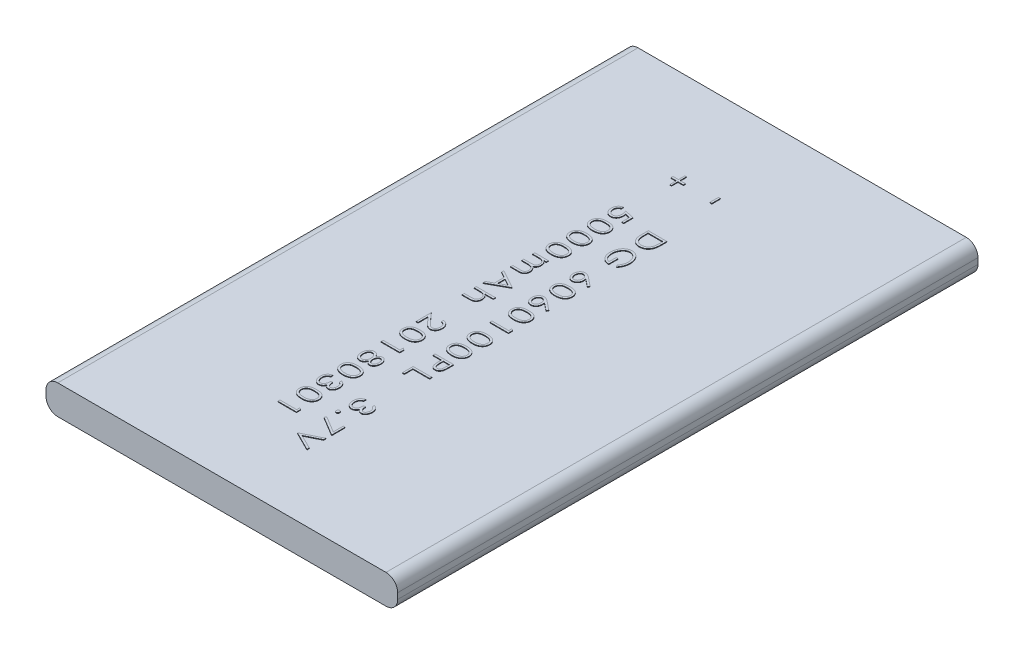
from build123d import *

# Parameters (mm, degrees)
SKETCH1_W           = 60
SKETCH1_H           = 99
BOSS_EXTRUDE1_DEPTH = 5
FILLET1_R           = 2
SKETCH7_W           = 0.325641026
SKETCH7_H           = 1.465384616
BOSS_EXTRUDE2_DEPTH = 0.1


with BuildPart() as part:
    # Sketch1 → Boss-Extrude1 (new body)
    with BuildSketch(Plane(origin=(0, 0, 0), x_dir=(1, 0, 0), z_dir=(0, 1, 0))):
        with Locations((4.498884589, -18.993992779)):
            Rectangle(SKETCH1_W, SKETCH1_H)
    extrude(amount=BOSS_EXTRUDE1_DEPTH)

    # Fillet1
    fillet1_edges = [part.edges().sort_by_distance(p)[0] for p in [
        (34.498884589, 5, 18.993992779),
        (-25.501115411, 5, 18.993992779),
        (34.498884589, 0, 18.993992779),
        (-25.501115411, 0, 18.993992779),
    ]]
    fillet(fillet1_edges, radius=FILLET1_R)

    # Sketch7 → Boss-Extrude2 (add)
    # profile 1 of 32: a face of its own
    with BuildSketch(Plane(origin=(0, 5, 0), x_dir=(1, 0, 0), z_dir=(0, 1, 0))):
        with Locations((5.720038435, 14.437129016)):
            Rectangle(SKETCH7_W, SKETCH7_H)
    # profile 2 of 32: a face of its own
    with BuildSketch(Plane(origin=(0, 5, 0), x_dir=(1, 0, 0), z_dir=(0, 1, 0))):
        with BuildLine():
            Line((4.498884589, 4.260846965), (7.673884589, 4.260846965))
            Line((7.673884589, 4.260846965), (7.673884589, 3.499533864))
            add(Edge.make_bspline(
                [(7.673884589, 3.499533864), (7.673484459, 3.43317292), (7.6727122, 3.305094904), (7.667789869, 3.120171902), (7.659125523, 2.949429436), (7.646347977, 2.792928984), (7.630926969, 2.650288789), (7.611315007, 2.521679529), (7.588546143, 2.407076906), (7.568710726, 2.336369601), (7.559401415, 2.303184705)],
                knots=[0, 0, 0, 0, 1.3211948, 2.549933714, 3.682670825, 4.72443222, 5.675778669, 6.538377397, 7.314020028, 8, 8, 8, 8], degree=3))
            add(Edge.make_bspline(
                [(7.559401415, 2.303184705), (7.545407951, 2.259708976), (7.517813808, 2.173977851), (7.466040509, 2.051073959), (7.406579295, 1.935634709), (7.34055876, 1.826672281), (7.26582248, 1.725953437), (7.185004361, 1.631351467), (7.095316874, 1.545707473), (6.999499407, 1.466631674), (6.897304398, 1.396304666), (6.790008086, 1.334707335), (6.677597349, 1.283441521), (6.560906844, 1.240176974), (6.438722772, 1.208098663), (6.312018278, 1.184786631), (6.180681168, 1.169378879), (6.091516569, 1.167970954), (6.046315478, 1.167257221)],
                knots=[0, 0, 0, 0, 1.07436122, 2.118565874, 3.133765883, 4.127984174, 5.11282082, 6.081965103, 7.052225859, 8.026990791, 9.002585186, 9.967895436, 10.934455346, 11.906676447, 12.892927292, 13.902719417, 14.936804816, 16, 16, 16, 16], degree=3))
            add(Edge.make_bspline(
                [(6.046315478, 1.167257221), (6.007073825, 1.168046427), (5.929712414, 1.169602276), (5.815481832, 1.180245017), (5.705076337, 1.199693084), (5.598166367, 1.225677464), (5.494374746, 1.258591507), (5.394702936, 1.300289289), (5.298131674, 1.348487055), (5.206338528, 1.404749627), (5.11885768, 1.465943391), (5.036978929, 1.532643269), (4.960810401, 1.603336276), (4.891176444, 1.679242023), (4.826634769, 1.758483289), (4.768718185, 1.842910431), (4.716464456, 1.931533855), (4.669444773, 2.025255648), (4.628216939, 2.12633264), (4.593682179, 2.236411614), (4.56459679, 2.355879285), (4.5405793, 2.484770787), (4.52156546, 2.623145495), (4.508634893, 2.771308708), (4.500060939, 2.928712359), (4.499283655, 3.036924953), (4.498884589, 3.092482582)],
                knots=[0, 0, 0, 0, 1.007617849, 1.9864285, 2.942247267, 3.883633272, 4.809833997, 5.734850137, 6.655096589, 7.578429292, 8.496677028, 9.394478445, 10.288044926, 11.162520667, 12.037352158, 12.910131862, 13.788664733, 14.677259388, 15.600206873, 16.588418372, 17.636741039, 18.755660717, 19.953576163, 21.221682691, 22.573578967, 24, 24, 24, 24], degree=3))
            Line((4.498884589, 3.092482582), (4.498884589, 4.260846965))
        make_face()
        with BuildLine():
            Line((4.824525614, 3.894500811), (4.824525614, 3.471549088))
            add(Edge.make_bspline(
                [(4.824525614, 3.471549088), (4.824749087, 3.410701279), (4.825178171, 3.293868872), (4.828983861, 3.125932293), (4.835187598, 2.972615628), (4.843881447, 2.83369295), (4.855313968, 2.709424092), (4.868230455, 2.599433262), (4.884114917, 2.50397393), (4.898609747, 2.445793265), (4.905299853, 2.418939914)],
                knots=[0, 0, 0, 0, 1.380201592, 2.650091708, 3.810045458, 4.860555721, 5.807075929, 6.640357142, 7.372455316, 8, 8, 8, 8], degree=3))
            add(Edge.make_bspline(
                [(4.905299853, 2.418939914), (4.915467346, 2.385300775), (4.935444521, 2.319206317), (4.972448062, 2.223775315), (5.015875833, 2.134306276), (5.064015483, 2.049625689), (5.119190032, 1.971225925), (5.179582719, 1.898083045), (5.24534444, 1.829995597), (5.317300812, 1.768544377), (5.39394599, 1.713160316), (5.475242004, 1.665431452), (5.560121817, 1.624229865), (5.649716994, 1.591341093), (5.74325083, 1.565126064), (5.840929931, 1.546810496), (5.942605201, 1.535852921), (6.011731042, 1.534362674), (6.046951496, 1.533603375)],
                knots=[0, 0, 0, 0, 1.078636083, 2.119313062, 3.13818688, 4.129559777, 5.106404306, 6.077267544, 7.039254257, 8.008545388, 8.978535547, 9.938516489, 10.899181185, 11.871221835, 12.864515792, 13.878074527, 14.918853268, 16, 16, 16, 16], degree=3))
            add(Edge.make_bspline(
                [(6.046951496, 1.533603375), (6.084085801, 1.534265729), (6.157075231, 1.535567621), (6.264306407, 1.547926948), (6.367210952, 1.568343763), (6.466089002, 1.596467253), (6.561417298, 1.631697229), (6.651898563, 1.676888813), (6.738621654, 1.728981858), (6.820917394, 1.78885184), (6.897406323, 1.856236116), (6.968816874, 1.929591855), (7.032654115, 2.01026577), (7.091816379, 2.096044889), (7.143047587, 2.189089893), (7.189193317, 2.28764617), (7.227947855, 2.393141853), (7.248655349, 2.466282022), (7.259201095, 2.503530258)],
                knots=[0, 0, 0, 0, 1.058669847, 2.080871278, 3.073316351, 4.047471421, 5.009847859, 5.967025571, 6.92717743, 7.89220902, 8.864786813, 9.831124328, 10.807453351, 11.795172645, 12.799353072, 13.832651409, 14.896230148, 16, 16, 16, 16], degree=3))
            add(Edge.make_bspline(
                [(7.259201095, 2.503530258), (7.266579166, 2.534405407), (7.282352403, 2.600411957), (7.299163138, 2.707416491), (7.314489714, 2.828088905), (7.32705631, 2.962570933), (7.336297691, 3.111266901), (7.343109172, 3.273697526), (7.347767635, 3.450109571), (7.348080947, 3.572248637), (7.348243563, 3.635641636)],
                knots=[0, 0, 0, 0, 0.669246088, 1.430750214, 2.28257198, 3.234651627, 4.278572046, 5.424227125, 6.663114321, 8, 8, 8, 8], degree=3))
            Line((7.348243563, 3.635641636), (7.348243563, 3.894500811))
            Line((7.348243563, 3.894500811), (4.824525614, 3.894500811))
        make_face(mode=Mode.SUBTRACT)
    # profile 3 of 32: a face of its own
    with BuildSketch(Plane(origin=(0, 5, 0), x_dir=(1, 0, 0), z_dir=(0, 1, 0))):
        with BuildLine():
            Line((7.131997569, -3.782486369), (6.900487153, -3.49246233))
            add(Edge.make_bspline(
                [(6.900487153, -3.49246233), (6.942107714, -3.440350497), (7.024703733, -3.336934546), (7.131781262, -3.170722264), (7.222282429, -2.996955385), (7.296968289, -2.817437769), (7.355966353, -2.635542038), (7.397908267, -2.454240346), (7.424938108, -2.275303937), (7.42809231, -2.156493559), (7.429653819, -2.097675671)],
                knots=[0, 0, 0, 0, 1.051690045, 2.087079233, 3.113373793, 4.138932281, 5.151205203, 6.126434174, 7.072478469, 8, 8, 8, 8], degree=3))
            add(Edge.make_bspline(
                [(7.429653819, -2.097675671), (7.429294385, -2.06161249), (7.42858072, -1.990008105), (7.418868688, -1.883283462), (7.405261486, -1.777717806), (7.385534993, -1.673439047), (7.359846444, -1.570518925), (7.328893463, -1.46894372), (7.291641768, -1.368626115), (7.249431891, -1.270329495), (7.202676857, -1.17500447), (7.151146375, -1.084814311), (7.095875008, -0.999789464), (7.035966014, -0.920871462), (6.972059698, -0.847519278), (6.904704626, -0.7790682), (6.832672384, -0.71675106), (6.757003852, -0.660321366), (6.679282147, -0.60970637), (6.600034558, -0.565197235), (6.519154433, -0.528662838), (6.43772452, -0.497735328), (6.354924354, -0.47411782), (6.271187309, -0.45695263), (6.186089338, -0.446339163), (6.129027904, -0.445225189), (6.100376976, -0.444665856)],
                knots=[0, 0, 0, 0, 1.105468341, 2.194936182, 3.283530858, 4.368567422, 5.447040496, 6.534877862, 7.622948302, 8.726675792, 9.814027425, 10.876789525, 11.909971167, 12.921533231, 13.912262658, 14.891406717, 15.863794094, 16.829836974, 17.783706843, 18.706224286, 19.613870379, 20.502577406, 21.37501437, 22.250908075, 23.121769257, 24, 24, 24, 24], degree=3))
            add(Edge.make_bspline(
                [(6.100376976, -0.444665856), (6.071087733, -0.445446001), (6.012526138, -0.447005841), (5.92531298, -0.458188647), (5.839180494, -0.475990727), (5.754020476, -0.500891499), (5.670118244, -0.533514065), (5.587254218, -0.573130347), (5.50544807, -0.619631068), (5.425980423, -0.673816445), (5.348325589, -0.733071508), (5.275095038, -0.799101819), (5.20570365, -0.869996757), (5.141345161, -0.947249112), (5.080145071, -1.028764223), (5.0241923, -1.116661968), (4.971874808, -1.209515583), (4.924489299, -1.307738933), (4.88232411, -1.409837533), (4.844271453, -1.514195015), (4.813261234, -1.621374309), (4.788035694, -1.731001764), (4.767182469, -1.842955894), (4.753859485, -1.957722285), (4.744188724, -2.074613508), (4.743474755, -2.15341255), (4.743115358, -2.193078316)],
                knots=[0, 0, 0, 0, 0.860089602, 1.719683201, 2.57817104, 3.441185742, 4.322317337, 5.219128001, 6.136645653, 7.083035128, 8.042020216, 9.003307018, 9.976439117, 10.953070987, 11.954323409, 12.968197319, 14.010859249, 15.083037173, 16.168869387, 17.254112285, 18.343776178, 19.443339951, 20.557197112, 21.686334613, 22.835349946, 24, 24, 24, 24], degree=3))
            add(Edge.make_bspline(
                [(4.743115358, -2.193078316), (4.743988554, -2.240808938), (4.74570706, -2.33474584), (4.758694861, -2.472626378), (4.779395343, -2.605106499), (4.809384559, -2.731765512), (4.847510354, -2.852991776), (4.894061133, -2.968792346), (4.949319883, -3.078819773), (5.012904559, -3.182307745), (5.082774218, -3.277911921), (5.158815358, -3.363733032), (5.239839178, -3.439026216), (5.325557832, -3.504777043), (5.416841725, -3.55944523), (5.513079942, -3.604389692), (5.614300846, -3.639317752), (5.684643151, -3.653323489), (5.720038435, -3.660370984)],
                knots=[0, 0, 0, 0, 1.194535948, 2.350922794, 3.463235178, 4.54827759, 5.60558648, 6.641234351, 7.668802615, 8.683562224, 9.678042673, 10.629028658, 11.548949685, 12.442583808, 13.328066836, 14.20644577, 15.097508097, 16, 16, 16, 16], degree=3))
            Line((5.720038435, -3.660370984), (5.720038435, -2.439217138))
            Line((5.720038435, -2.439217138), (6.04567946, -2.439217138))
            Line((6.04567946, -2.439217138), (6.04567946, -4.026717138))
            add(Edge.make_bspline(
                [(6.04567946, -4.026717138), (5.984959759, -4.02493441), (5.865971838, -4.021440931), (5.692484735, -3.996226942), (5.528604821, -3.955552895), (5.374360609, -3.899424997), (5.229539317, -3.827871673), (5.094452635, -3.740350141), (4.969918454, -3.636064318), (4.854813368, -3.518131244), (4.75204296, -3.386259513), (4.662041937, -3.243330352), (4.585927676, -3.089695103), (4.524396621, -2.925260857), (4.475920193, -2.75034616), (4.442036396, -2.564742619), (4.421397492, -2.368663328), (4.418803264, -2.234471364), (4.417474332, -2.165729558)],
                knots=[0, 0, 0, 0, 1.0455947, 2.048974812, 3.012542145, 3.949398629, 4.87043009, 5.789069728, 6.71478708, 7.662482978, 8.622313725, 9.588817158, 10.56700413, 11.570071904, 12.608372293, 13.68911484, 14.816215109, 16, 16, 16, 16], degree=3))
            add(Edge.make_bspline(
                [(4.417474332, -2.165729558), (4.417991253, -2.123529794), (4.419012814, -2.040132806), (4.426279276, -1.916667458), (4.437304436, -1.796501687), (4.454232946, -1.679657154), (4.474775174, -1.565994009), (4.50100419, -1.455897118), (4.531763757, -1.349214549), (4.566310194, -1.245594388), (4.606713718, -1.145571231), (4.651271467, -1.048782487), (4.69998696, -0.955055659), (4.754472939, -0.865356663), (4.812892799, -0.778459469), (4.876776806, -0.695330808), (4.944460883, -0.61486188), (4.993393028, -0.564586487), (5.017874973, -0.539432482)],
                knots=[0, 0, 0, 0, 1.1371443, 2.247273499, 3.331942681, 4.387946523, 5.427831979, 6.443582453, 7.436305077, 8.41913104, 9.385614499, 10.341673777, 11.289745042, 12.230350519, 13.168419401, 14.109978672, 15.054376264, 16, 16, 16, 16], degree=3))
            add(Edge.make_bspline(
                [(5.017874973, -0.539432482), (5.05639532, -0.502582878), (5.132111324, -0.430150902), (5.255844255, -0.337084254), (5.382736043, -0.256414183), (5.515004493, -0.191327654), (5.651922152, -0.14084824), (5.793137391, -0.104462419), (5.938960172, -0.082103515), (6.037756278, -0.079589494), (6.087656624, -0.078319702)],
                knots=[0, 0, 0, 0, 1.068142104, 2.099551513, 3.098631209, 4.079702073, 5.049507175, 6.019806027, 6.999835448, 8, 8, 8, 8], degree=3))
            add(Edge.make_bspline(
                [(6.087656624, -0.078319702), (6.125011185, -0.078924196), (6.199306673, -0.080126491), (6.309559399, -0.093757197), (6.417885541, -0.11363006), (6.524116893, -0.142711927), (6.628415697, -0.179388821), (6.730686561, -0.225119518), (6.831213062, -0.278319846), (6.928818119, -0.340307088), (7.023404512, -0.40833615), (7.112454085, -0.483869929), (7.196832502, -0.564781396), (7.275639716, -0.651952564), (7.349088737, -0.745288431), (7.417198638, -0.844772303), (7.480152488, -0.950306707), (7.537246228, -1.061732798), (7.588590778, -1.177607335), (7.633498029, -1.297735924), (7.670504624, -1.421773409), (7.702348467, -1.549365047), (7.72526436, -1.681026583), (7.742449609, -1.816417446), (7.753837059, -1.955437032), (7.754805717, -2.049527983), (7.755294845, -2.097039654)],
                knots=[0, 0, 0, 0, 0.922116276, 1.834021798, 2.739818267, 3.640408486, 4.551276102, 5.467860093, 6.404842559, 7.35785538, 8.321454379, 9.280189675, 10.239339559, 11.206913935, 12.180082907, 13.170621294, 14.182682543, 15.213107843, 16.261013199, 17.311453488, 18.378236868, 19.456460509, 20.557544245, 21.676597022, 22.826786682, 24, 24, 24, 24], degree=3))
            add(Edge.make_bspline(
                [(7.755294845, -2.097039654), (7.754763177, -2.135635003), (7.753704829, -2.212463554), (7.746519799, -2.326829425), (7.735105834, -2.439492822), (7.719346548, -2.550538255), (7.698224711, -2.659772409), (7.67279751, -2.767362276), (7.642915813, -2.873337691), (7.607852821, -2.977750028), (7.567739061, -3.080898812), (7.52229762, -3.183183786), (7.471477064, -3.28490439), (7.414701708, -3.386069911), (7.352549347, -3.486614033), (7.283847695, -3.585776869), (7.211126589, -3.685365881), (7.158583306, -3.749855866), (7.131997569, -3.782486369)],
                knots=[0, 0, 0, 0, 1.0086412, 2.007818129, 2.993570637, 3.967543191, 4.937915912, 5.900155721, 6.856057776, 7.814461525, 8.777530466, 9.747396878, 10.738537876, 11.748122144, 12.778265293, 13.826385183, 14.900199092, 16, 16, 16, 16], degree=3))
        make_face()
    # profile 4 of 32: a face of its own
    with BuildSketch(Plane(origin=(0, 5, 0), x_dir=(1, 0, 0), z_dir=(0, 1, 0))):
        with BuildLine():
            Line((7.755294845, -8.919473548), (7.582934068, -9.224125992))
            Line((7.582934068, -9.224125992), (6.295634388, -8.198229558))
            add(Edge.make_bspline(
                [(6.295634388, -8.198229558), (6.301025331, -8.231685828), (6.311575651, -8.297161266), (6.322002069, -8.394394385), (6.329795894, -8.488338592), (6.330345583, -8.550143712), (6.330615358, -8.580476152)],
                knots=[0, 0, 0, 0, 1.058010251, 2.070574033, 3.053084957, 4, 4, 4, 4], degree=3))
            add(Edge.make_bspline(
                [(6.330615358, -8.580476152), (6.329749104, -8.617192097), (6.328046321, -8.689364137), (6.314952964, -8.795305283), (6.294206636, -8.897142709), (6.264145646, -8.994598743), (6.225900177, -9.087878777), (6.179173981, -9.176970709), (6.123640382, -9.261617119), (6.060412721, -9.341215451), (5.991316113, -9.413993746), (5.916794609, -9.477212898), (5.839476985, -9.532061204), (5.756827952, -9.575332631), (5.670923987, -9.610189375), (5.580504993, -9.634076405), (5.486494772, -9.649235772), (5.422440982, -9.651179676), (5.389945286, -9.652165856)],
                knots=[0, 0, 0, 0, 1.109825524, 2.181569119, 3.222467771, 4.248417288, 5.260212319, 6.266591961, 7.285307335, 8.316410101, 9.336475716, 10.314006014, 11.267104832, 12.196169053, 13.12816955, 14.064217079, 15.017940773, 16, 16, 16, 16], degree=3))
            add(Edge.make_bspline(
                [(5.389945286, -9.652165856), (5.367453253, -9.651649151), (5.322997104, -9.650627868), (5.257126471, -9.643323746), (5.192840363, -9.632140635), (5.130241061, -9.615620846), (5.069768483, -9.59347921), (5.010166723, -9.568276134), (4.952297529, -9.537652409), (4.896389746, -9.502089617), (4.843234749, -9.461818788), (4.791908024, -9.418470675), (4.743368323, -9.371035936), (4.699356074, -9.31812335), (4.656033661, -9.263072578), (4.617004353, -9.202884599), (4.579899609, -9.139394244), (4.535131477, -9.04930636), (4.48799175, -8.931248485), (4.447080088, -8.783517757), (4.422265643, -8.630499369), (4.419083012, -8.526718088), (4.417474332, -8.474261208)],
                knots=[0, 0, 0, 0, 0.793610774, 1.568594449, 2.33613927, 3.094698069, 3.849595439, 4.607009634, 5.376739122, 6.157120937, 6.942685696, 7.728214828, 8.527062853, 9.333685654, 10.155228717, 10.997694596, 11.862584698, 12.749237447, 14.5455932, 16.338939522, 18.14949471, 20, 20, 20, 20], degree=3))
            add(Edge.make_bspline(
                [(4.417474332, -8.474261208), (4.418869848, -8.423502899), (4.421629642, -8.323122478), (4.445739871, -8.175604882), (4.485651857, -8.033941615), (4.53077059, -7.920846352), (4.575053203, -7.835103251), (4.61111487, -7.773972267), (4.650837317, -7.716532098), (4.693317008, -7.662383819), (4.739208558, -7.611971109), (4.788518158, -7.565455042), (4.840569198, -7.522032628), (4.896008025, -7.482751894), (4.953292211, -7.447325409), (5.01208692, -7.416783003), (5.071505002, -7.390477171), (5.131989517, -7.368671286), (5.1937026, -7.352137059), (5.256478002, -7.340797504), (5.320027204, -7.333565688), (5.362789511, -7.332505096), (5.384221127, -7.331973548)],
                knots=[0, 0, 0, 0, 1.829166724, 3.617388518, 5.371883585, 7.127710212, 7.996045927, 8.849450176, 9.684829182, 10.512125839, 11.329153507, 12.140187919, 12.95445771, 13.771056192, 14.587797761, 15.380985848, 16.157874576, 16.929140029, 17.69676061, 18.458382721, 19.227372154, 20, 20, 20, 20], degree=3))
            add(Edge.make_bspline(
                [(5.384221127, -7.331973548), (5.416942702, -7.333092773), (5.483909653, -7.335383343), (5.585255352, -7.354105446), (5.688744366, -7.384575472), (5.77627024, -7.418620542), (5.848216937, -7.453205067), (5.905857216, -7.48350161), (5.966042228, -7.518864158), (6.028793973, -7.559117431), (6.094789951, -7.603290024), (6.163123148, -7.652738988), (6.234162274, -7.706606688), (6.281940744, -7.744850163), (6.306446688, -7.764465535)],
                knots=[0, 0, 0, 0, 1.133647484, 2.320087505, 3.559685757, 4.869774462, 5.569919621, 6.325990228, 7.126335854, 7.988686501, 8.909958631, 9.878720016, 10.9119792, 12, 12, 12, 12], degree=3))
            Line((6.306446688, -7.764465535), (7.755294845, -8.919473548))
        make_face()
        with BuildLine():
            add(Edge.make_bspline(
                [(6.004974332, -8.493341737), (6.004258255, -8.466401703), (6.002850935, -8.413455904), (5.994883748, -8.33549762), (5.979724719, -8.260817945), (5.960538103, -8.188627743), (5.934155858, -8.119769944), (5.902126503, -8.053870808), (5.86464044, -7.99075543), (5.821592192, -7.931598635), (5.775046284, -7.876867718), (5.724830489, -7.82926775), (5.672440496, -7.788546759), (5.61720042, -7.75590335), (5.559587132, -7.730238714), (5.49963805, -7.711681227), (5.436997644, -7.700557449), (5.394442506, -7.699074726), (5.37277281, -7.698319702)],
                knots=[0, 0, 0, 0, 1.148408277, 2.256990234, 3.334386658, 4.393132075, 5.43692792, 6.471453079, 7.512782197, 8.561065829, 9.586196649, 10.570453501, 11.504795903, 12.408218857, 13.298120773, 14.186967025, 15.076777194, 16, 16, 16, 16], degree=3))
            add(Edge.make_bspline(
                [(5.37277281, -7.698319702), (5.351307254, -7.699049983), (5.309157827, -7.700483951), (5.247114826, -7.711985989), (5.187270081, -7.729289251), (5.129973486, -7.755428424), (5.075222022, -7.788391502), (5.023418636, -7.829479551), (4.972810329, -7.876191109), (4.926516664, -7.930992195), (4.883626149, -7.990013307), (4.845849459, -8.052726617), (4.813734214, -8.118354989), (4.788559179, -8.187613186), (4.768103063, -8.259409058), (4.753281559, -8.334248003), (4.745218824, -8.412177959), (4.743824713, -8.465127675), (4.743115358, -8.492069702)],
                knots=[0, 0, 0, 0, 0.916838459, 1.800289591, 2.689069047, 3.573263434, 4.483946284, 5.413812901, 6.394690206, 7.422776304, 8.47408196, 9.510639307, 10.548146826, 11.591770033, 12.65600087, 13.736503246, 14.848281056, 16, 16, 16, 16], degree=3))
            add(Edge.make_bspline(
                [(4.743115358, -8.492069702), (4.743818716, -8.519012983), (4.745201042, -8.571965162), (4.753370689, -8.650084493), (4.767908416, -8.724988643), (4.788667772, -8.796713266), (4.813879362, -8.865921855), (4.845668984, -8.931926012), (4.883650806, -8.994747844), (4.926500973, -9.053798895), (4.972847083, -9.108537888), (5.023200905, -9.155366113), (5.075440209, -9.195676577), (5.129945935, -9.228746604), (5.187277412, -9.254840674), (5.247112883, -9.272155927), (5.309158333, -9.283654798), (5.351307425, -9.2850892), (5.37277281, -9.285819702)],
                knots=[0, 0, 0, 0, 1.151517375, 2.263100608, 3.352305185, 4.407635402, 5.451075959, 6.496559859, 7.532935794, 8.584057455, 9.611963622, 10.592669259, 11.516838475, 12.427361942, 13.311401581, 14.200025487, 15.083322001, 16, 16, 16, 16], degree=3))
            add(Edge.make_bspline(
                [(5.37277281, -9.285819702), (5.394447386, -9.285081999), (5.437012107, -9.283633291), (5.499521945, -9.272272595), (5.559677435, -9.254676142), (5.617401067, -9.228961095), (5.672061495, -9.195451746), (5.72485519, -9.155602915), (5.77521686, -9.108503091), (5.82159492, -9.053807561), (5.864441077, -8.994749661), (5.902307139, -8.932074004), (5.934141486, -8.866264511), (5.960419658, -8.797601072), (5.979828717, -8.725681736), (5.994866153, -8.651181214), (6.002855573, -8.573228794), (6.004259819, -8.520282184), (6.004974332, -8.493341737)],
                knots=[0, 0, 0, 0, 0.924732328, 1.815997387, 2.703671035, 3.595027991, 4.504577782, 5.434961697, 6.414618607, 7.441425573, 8.491423209, 9.526690886, 10.562907551, 11.608410062, 12.66016143, 13.739319459, 14.84971401, 16, 16, 16, 16], degree=3))
        make_face(mode=Mode.SUBTRACT)
    # profile 5 of 32: a face of its own
    with BuildSketch(Plane(origin=(0, 5, 0), x_dir=(1, 0, 0), z_dir=(0, 1, 0))):
        with BuildLine():
            add(Edge.make_bspline(
                [(6.085112553, -10.694217138), (6.136006671, -10.694648876), (6.23488693, -10.695487682), (6.378898877, -10.703586846), (6.514193014, -10.714829006), (6.640385424, -10.733028808), (6.757705006, -10.754824422), (6.866087329, -10.782091222), (6.965679269, -10.814283401), (7.056735196, -10.852133738), (7.14051863, -10.894679391), (7.21912669, -10.940122739), (7.291964461, -10.990933784), (7.360013779, -11.045277176), (7.422482113, -11.104213186), (7.480259028, -11.166457027), (7.531542091, -11.233862034), (7.57883348, -11.304077231), (7.619943574, -11.378159585), (7.656313367, -11.454321305), (7.686940731, -11.532759909), (7.711716598, -11.61338736), (7.731568267, -11.69598032), (7.745441135, -11.780791621), (7.754023808, -11.867702262), (7.754867672, -11.926375193), (7.755294845, -11.956076112)],
                knots=[0, 0, 0, 0, 1.542683654, 2.997221792, 4.371598944, 5.656797318, 6.860561199, 7.987553175, 9.042377021, 10.030645594, 10.973394823, 11.889388256, 12.780791065, 13.663064894, 14.526958713, 15.382106205, 16.234399085, 17.091789701, 17.946381534, 18.800199673, 19.648776936, 20.49647757, 21.355408439, 22.221808829, 23.099858982, 24, 24, 24, 24], degree=3))
            add(Edge.make_bspline(
                [(7.755294845, -11.956076112), (7.754867482, -11.986200763), (7.75402312, -12.045719438), (7.745440273, -12.133898873), (7.731570155, -12.21997979), (7.711713085, -12.30383977), (7.686959657, -12.385746351), (7.656270057, -12.465417302), (7.620104069, -12.543086134), (7.578012599, -12.617985927), (7.530945904, -12.690423963), (7.477607625, -12.758799732), (7.418715226, -12.823212816), (7.354885419, -12.88422465), (7.284726454, -12.9404577), (7.209444728, -12.993568004), (7.128392135, -13.042492387), (7.041655621, -13.087816078), (6.948431331, -13.128936406), (6.847552854, -13.163749757), (6.739072144, -13.192774297), (6.623108303, -13.216780809), (6.499380566, -13.236003051), (6.367929133, -13.248776173), (6.228969917, -13.257478194), (6.133888239, -13.258246225), (6.085112553, -13.258640215)],
                knots=[0, 0, 0, 0, 0.905226779, 1.788498657, 2.660108446, 3.524138063, 4.376813936, 5.230061085, 6.088148717, 6.949707488, 7.810441066, 8.682307051, 9.552891307, 10.431831136, 11.333484681, 12.252799274, 13.19921049, 14.17683564, 15.192654415, 16.258736151, 17.380986388, 18.565756088, 19.816677794, 21.14251623, 22.534147352, 24, 24, 24, 24], degree=3))
            add(Edge.make_bspline(
                [(6.085112553, -13.258640215), (6.036549354, -13.258241942), (5.941892278, -13.257465648), (5.803560957, -13.248825548), (5.672802812, -13.235840604), (5.54969216, -13.217374389), (5.43422664, -13.194268613), (5.326446791, -13.164698387), (5.225775921, -13.131034193), (5.133040799, -13.090333195), (5.046931501, -13.045673059), (4.966244642, -12.997256149), (4.891191363, -12.944301721), (4.821086281, -12.887798183), (4.756375003, -12.827245287), (4.69792264, -12.761983043), (4.644244607, -12.693349139), (4.596539312, -12.620722356), (4.554745587, -12.544798385), (4.51770873, -12.467026402), (4.487165422, -12.38670838), (4.461624687, -12.304779587), (4.441737849, -12.220409532), (4.42823645, -12.134061954), (4.418518884, -12.045762386), (4.417825273, -11.986208256), (4.417474332, -11.956076112)],
                knots=[0, 0, 0, 0, 1.460743023, 2.84721075, 4.167850277, 5.412587228, 6.590844802, 7.707910044, 8.772833715, 9.781134206, 10.751002957, 11.689474493, 12.609583831, 13.512016852, 14.396351346, 15.272413723, 16.145033432, 17.015342675, 17.883218137, 18.750530986, 19.604515764, 20.465899004, 21.330675571, 22.209334244, 23.093990656, 24, 24, 24, 24], degree=3))
            add(Edge.make_bspline(
                [(4.417474332, -11.956076112), (4.417903861, -11.926375623), (4.418752378, -11.867703541), (4.427300955, -11.780786679), (4.441259138, -11.696250253), (4.460546749, -11.6138758), (4.48424924, -11.533430367), (4.515363839, -11.45575829), (4.55085175, -11.380050308), (4.591414392, -11.306645009), (4.638161446, -11.236757594), (4.689408725, -11.169718347), (4.74686187, -11.107108656), (4.810419627, -11.049598402), (4.877657243, -10.994241767), (4.951345057, -10.944085517), (5.030292877, -10.897805837), (5.114757272, -10.85467931), (5.206445459, -10.816234276), (5.306560112, -10.783148297), (5.415604274, -10.756438779), (5.532718136, -10.733411724), (5.658626985, -10.715742502), (5.793187367, -10.703320842), (5.936405335, -10.695571659), (6.034644956, -10.694676829), (6.085112553, -10.694217138)],
                knots=[0, 0, 0, 0, 0.901313614, 1.780507586, 2.648036619, 3.500347198, 4.347271604, 5.190962528, 6.037324413, 6.884273269, 7.733858471, 8.587261616, 9.443523092, 10.308877354, 11.187293768, 12.085154678, 13.011148997, 13.963773228, 14.961747202, 16.026069565, 17.160769593, 18.367320705, 19.647821669, 21.018168876, 22.468175576, 24, 24, 24, 24], degree=3))
        make_face()
        with BuildLine():
            add(Edge.make_bspline(
                [(6.086384589, -11.060563292), (6.043979271, -11.060971698), (5.96168137, -11.06176431), (5.842021215, -11.066659037), (5.730450532, -11.07558234), (5.626843664, -11.087400085), (5.531276783, -11.103148358), (5.443596681, -11.122776415), (5.363857684, -11.145458359), (5.291528328, -11.171715617), (5.225633282, -11.201956578), (5.164261798, -11.23516361), (5.106944615, -11.271290478), (5.053676192, -11.310945229), (5.004764061, -11.354355329), (4.959434407, -11.400689039), (4.918384505, -11.450723251), (4.870280522, -11.521059204), (4.819034647, -11.61264468), (4.775838966, -11.728055398), (4.748237417, -11.846659599), (4.744828714, -11.927094501), (4.743115358, -11.967524429)],
                knots=[0, 0, 0, 0, 1.388587631, 2.694894295, 3.920573386, 5.05291137, 6.108598713, 7.090490714, 7.993531689, 8.82151309, 9.607480571, 10.365416635, 11.104976342, 11.824185169, 12.537337675, 13.244279737, 13.944715534, 14.653359842, 16.032946572, 17.368730189, 18.677414287, 20, 20, 20, 20], degree=3))
            add(Edge.make_bspline(
                [(4.743115358, -11.967524429), (4.744531096, -12.008176858), (4.747340909, -12.088859684), (4.775307339, -12.207032069), (4.817062716, -12.321716518), (4.867054602, -12.412238077), (4.914574313, -12.481160518), (4.955223079, -12.530104528), (5.000084848, -12.575692324), (5.04968667, -12.617615409), (5.102350967, -12.657726558), (5.16055758, -12.69275814), (5.2223798, -12.725706843), (5.265979535, -12.744216351), (5.288182465, -12.753642218)],
                knots=[0, 0, 0, 0, 1.435202654, 2.84844493, 4.271653763, 5.741104123, 6.489771913, 7.229832304, 7.987899838, 8.748188279, 9.524858768, 10.325895147, 11.147471145, 12, 12, 12, 12], degree=3))
            add(Edge.make_bspline(
                [(5.288182465, -12.753642218), (5.316458799, -12.764826604), (5.373676947, -12.7874586), (5.463317457, -12.814971796), (5.556536071, -12.83953742), (5.654386707, -12.858119656), (5.756178133, -12.873693724), (5.862560013, -12.884010557), (5.973063646, -12.891605536), (6.048209619, -12.892062114), (6.086384589, -12.892294061)],
                knots=[0, 0, 0, 0, 0.89477914, 1.810616812, 2.758161515, 3.731176502, 4.7408655, 5.788454827, 6.876511068, 8, 8, 8, 8], degree=3))
            add(Edge.make_bspline(
                [(6.086384589, -12.892294061), (6.124553837, -12.891949075), (6.199240748, -12.891274032), (6.308495459, -12.885389019), (6.412543266, -12.876260111), (6.511121717, -12.861904369), (6.604598138, -12.845092395), (6.692859426, -12.824304489), (6.775467317, -12.798545933), (6.853425794, -12.770257805), (6.925678401, -12.737724033), (6.993080346, -12.702589651), (7.055490762, -12.664548344), (7.112988492, -12.623173983), (7.165139012, -12.578532129), (7.212652829, -12.531371014), (7.254643845, -12.481002967), (7.303466486, -12.410923399), (7.352955677, -12.319120068), (7.39815744, -12.20522315), (7.424188823, -12.087202064), (7.42782828, -12.007501796), (7.429653819, -11.967524429)],
                knots=[0, 0, 0, 0, 1.249780456, 2.445482825, 3.581852642, 4.668687876, 5.706271375, 6.691314309, 7.63556384, 8.538297997, 9.405302693, 10.228187559, 11.02591342, 11.796629424, 12.545106863, 13.271626958, 13.986275284, 14.689228451, 16.065495506, 17.390812878, 18.691241169, 20, 20, 20, 20], degree=3))
            add(Edge.make_bspline(
                [(7.429653819, -11.967524429), (7.427842104, -11.926909217), (7.42423984, -11.846153305), (7.398198604, -11.726890549), (7.353390218, -11.612299729), (7.303036057, -11.521161528), (7.255720698, -11.451131681), (7.214333171, -11.401988892), (7.169553925, -11.355528052), (7.119921372, -11.312972428), (7.067353361, -11.272438704), (7.009733789, -11.23650067), (6.948437605, -11.203164526), (6.882370386, -11.173157391), (6.810341184, -11.145875408), (6.73060642, -11.123596552), (6.643023342, -11.103550787), (6.547136532, -11.088275878), (6.443428562, -11.075404679), (6.33159069, -11.066674978), (6.211725278, -11.061755864), (6.129002463, -11.060968785), (6.086384589, -11.060563292)],
                knots=[0, 0, 0, 0, 1.329473786, 2.643415121, 3.97515249, 5.345273436, 6.044244214, 6.739308648, 7.44623188, 8.154789303, 8.878154807, 9.617694816, 10.37561069, 11.161557236, 11.991928558, 12.894945479, 13.870039332, 14.932546687, 16.072574108, 17.291300563, 18.604508161, 20, 20, 20, 20], degree=3))
        make_face(mode=Mode.SUBTRACT)
    # profile 6 of 32: a face of its own
    with BuildSketch(Plane(origin=(0, 5, 0), x_dir=(1, 0, 0), z_dir=(0, 1, 0))):
        with BuildLine():
            Line((7.755294845, -15.969601753), (7.582934068, -16.274254197))
            Line((7.582934068, -16.274254197), (6.295634388, -15.248357763))
            add(Edge.make_bspline(
                [(6.295634388, -15.248357763), (6.301025331, -15.281814033), (6.311575651, -15.347289471), (6.322002069, -15.44452259), (6.329795894, -15.538466797), (6.330345583, -15.600271917), (6.330615358, -15.630604357)],
                knots=[0, 0, 0, 0, 1.058010251, 2.070574033, 3.053084957, 4, 4, 4, 4], degree=3))
            add(Edge.make_bspline(
                [(6.330615358, -15.630604357), (6.329749104, -15.667320302), (6.328046321, -15.739492342), (6.314952964, -15.845433488), (6.294206636, -15.947270915), (6.264145646, -16.044726948), (6.225900177, -16.138006982), (6.179173981, -16.227098914), (6.123640382, -16.311745324), (6.060412721, -16.391343656), (5.991316113, -16.464121951), (5.916794609, -16.527341103), (5.839476985, -16.582189409), (5.756827952, -16.625460837), (5.670923987, -16.66031758), (5.580504993, -16.68420461), (5.486494772, -16.699363978), (5.422440982, -16.701307882), (5.389945286, -16.702294061)],
                knots=[0, 0, 0, 0, 1.109825524, 2.181569119, 3.222467771, 4.248417288, 5.260212319, 6.266591961, 7.285307335, 8.316410101, 9.336475716, 10.314006014, 11.267104832, 12.196169053, 13.12816955, 14.064217079, 15.017940773, 16, 16, 16, 16], degree=3))
            add(Edge.make_bspline(
                [(5.389945286, -16.702294061), (5.367453253, -16.701777356), (5.322997104, -16.700756073), (5.257126471, -16.693451951), (5.192840363, -16.68226884), (5.130241061, -16.665749051), (5.069768483, -16.643607415), (5.010166723, -16.61840434), (4.952297529, -16.587780614), (4.896389746, -16.552217822), (4.843234749, -16.511946993), (4.791908024, -16.46859888), (4.743368323, -16.421164141), (4.699356074, -16.368251555), (4.656033661, -16.313200783), (4.617004353, -16.253012804), (4.579899609, -16.189522449), (4.535131477, -16.099434566), (4.48799175, -15.98137669), (4.447080088, -15.833645962), (4.422265643, -15.680627574), (4.419083012, -15.576846293), (4.417474332, -15.524389413)],
                knots=[0, 0, 0, 0, 0.793610774, 1.568594449, 2.33613927, 3.094698069, 3.849595439, 4.607009634, 5.376739122, 6.157120937, 6.942685696, 7.728214828, 8.527062853, 9.333685654, 10.155228717, 10.997694596, 11.862584698, 12.749237447, 14.5455932, 16.338939522, 18.14949471, 20, 20, 20, 20], degree=3))
            add(Edge.make_bspline(
                [(4.417474332, -15.524389413), (4.418869848, -15.473631104), (4.421629642, -15.373250683), (4.445739871, -15.225733088), (4.485651857, -15.08406982), (4.53077059, -14.970974558), (4.575053203, -14.885231456), (4.61111487, -14.824100472), (4.650837317, -14.766660303), (4.693317008, -14.712512024), (4.739208558, -14.662099314), (4.788518158, -14.615583247), (4.840569198, -14.572160833), (4.896008025, -14.532880099), (4.953292211, -14.497453614), (5.01208692, -14.466911208), (5.071505002, -14.440605376), (5.131989517, -14.418799491), (5.1937026, -14.402265264), (5.256478002, -14.390925709), (5.320027204, -14.383693893), (5.362789511, -14.382633301), (5.384221127, -14.382101753)],
                knots=[0, 0, 0, 0, 1.829166724, 3.617388518, 5.371883585, 7.127710212, 7.996045927, 8.849450176, 9.684829182, 10.512125839, 11.329153507, 12.140187919, 12.95445771, 13.771056192, 14.587797761, 15.380985848, 16.157874576, 16.929140029, 17.69676061, 18.458382721, 19.227372154, 20, 20, 20, 20], degree=3))
            add(Edge.make_bspline(
                [(5.384221127, -14.382101753), (5.416942702, -14.383220978), (5.483909653, -14.385511548), (5.585255352, -14.404233651), (5.688744366, -14.434703677), (5.77627024, -14.468748748), (5.848216937, -14.503333272), (5.905857216, -14.533629815), (5.966042228, -14.568992363), (6.028793973, -14.609245636), (6.094789951, -14.653418229), (6.163123148, -14.702867193), (6.234162274, -14.756734893), (6.281940744, -14.794978368), (6.306446688, -14.81459374)],
                knots=[0, 0, 0, 0, 1.133647484, 2.320087505, 3.559685757, 4.869774462, 5.569919621, 6.325990228, 7.126335854, 7.988686501, 8.909958631, 9.878720016, 10.9119792, 12, 12, 12, 12], degree=3))
            Line((6.306446688, -14.81459374), (7.755294845, -15.969601753))
        make_face()
        with BuildLine():
            add(Edge.make_bspline(
                [(6.004974332, -15.543469942), (6.004258255, -15.516529908), (6.002850935, -15.463584109), (5.994883748, -15.385625825), (5.979724719, -15.31094615), (5.960538103, -15.238755949), (5.934155858, -15.169898149), (5.902126503, -15.103999013), (5.86464044, -15.040883636), (5.821592192, -14.98172684), (5.775046284, -14.926995923), (5.724830489, -14.879395955), (5.672440496, -14.838674965), (5.61720042, -14.806031555), (5.559587132, -14.780366919), (5.49963805, -14.761809432), (5.436997644, -14.750685654), (5.394442506, -14.749202931), (5.37277281, -14.748447907)],
                knots=[0, 0, 0, 0, 1.148408277, 2.256990234, 3.334386658, 4.393132075, 5.43692792, 6.471453079, 7.512782197, 8.561065829, 9.586196649, 10.570453501, 11.504795903, 12.408218857, 13.298120773, 14.186967025, 15.076777194, 16, 16, 16, 16], degree=3))
            add(Edge.make_bspline(
                [(5.37277281, -14.748447907), (5.351307254, -14.749178188), (5.309157827, -14.750612156), (5.247114826, -14.762114194), (5.187270081, -14.779417456), (5.129973486, -14.805556629), (5.075222022, -14.838519707), (5.023418636, -14.879607756), (4.972810329, -14.926319315), (4.926516664, -14.9811204), (4.883626149, -15.040141512), (4.845849459, -15.102854822), (4.813734214, -15.168483194), (4.788559179, -15.237741391), (4.768103063, -15.309537264), (4.753281559, -15.384376208), (4.745218824, -15.462306164), (4.743824713, -15.51525588), (4.743115358, -15.542197907)],
                knots=[0, 0, 0, 0, 0.916838459, 1.800289591, 2.689069047, 3.573263434, 4.483946284, 5.413812901, 6.394690206, 7.422776304, 8.47408196, 9.510639307, 10.548146826, 11.591770033, 12.65600087, 13.736503246, 14.848281056, 16, 16, 16, 16], degree=3))
            add(Edge.make_bspline(
                [(4.743115358, -15.542197907), (4.743818716, -15.569141188), (4.745201042, -15.622093367), (4.753370689, -15.700212698), (4.767908416, -15.775116848), (4.788667772, -15.846841471), (4.813879362, -15.91605006), (4.845668984, -15.982054217), (4.883650806, -16.044876049), (4.926500973, -16.1039271), (4.972847083, -16.158666093), (5.023200905, -16.205494319), (5.075440209, -16.245804782), (5.129945935, -16.278874809), (5.187277412, -16.304968879), (5.247112883, -16.322284133), (5.309158333, -16.333783003), (5.351307425, -16.335217405), (5.37277281, -16.335947907)],
                knots=[0, 0, 0, 0, 1.151517375, 2.263100608, 3.352305185, 4.407635402, 5.451075959, 6.496559859, 7.532935794, 8.584057455, 9.611963622, 10.592669259, 11.516838475, 12.427361942, 13.311401581, 14.200025487, 15.083322001, 16, 16, 16, 16], degree=3))
            add(Edge.make_bspline(
                [(5.37277281, -16.335947907), (5.394447386, -16.335210204), (5.437012107, -16.333761496), (5.499521945, -16.3224008), (5.559677435, -16.304804347), (5.617401067, -16.2790893), (5.672061495, -16.245579951), (5.72485519, -16.20573112), (5.77521686, -16.158631296), (5.82159492, -16.103935766), (5.864441077, -16.044877866), (5.902307139, -15.982202209), (5.934141486, -15.916392716), (5.960419658, -15.847729277), (5.979828717, -15.775809941), (5.994866153, -15.701309419), (6.002855573, -15.623356999), (6.004259819, -15.570410389), (6.004974332, -15.543469942)],
                knots=[0, 0, 0, 0, 0.924732328, 1.815997387, 2.703671035, 3.595027991, 4.504577782, 5.434961697, 6.414618607, 7.441425573, 8.491423209, 9.526690886, 10.562907551, 11.608410062, 12.66016143, 13.739319459, 14.84971401, 16, 16, 16, 16], degree=3))
        make_face(mode=Mode.SUBTRACT)
    # profile 7 of 32: a face of its own
    with BuildSketch(Plane(origin=(0, 5, 0), x_dir=(1, 0, 0), z_dir=(0, 1, 0))):
        with BuildLine():
            add(Edge.make_bspline(
                [(6.085112553, -17.744345343), (6.136006671, -17.744777081), (6.23488693, -17.745615888), (6.378898877, -17.753715051), (6.514193014, -17.764957211), (6.640385424, -17.783157014), (6.757705006, -17.804952627), (6.866087329, -17.832219427), (6.965679269, -17.864411606), (7.056735196, -17.902261943), (7.14051863, -17.944807597), (7.21912669, -17.990250944), (7.291964461, -18.04106199), (7.360013779, -18.095405381), (7.422482113, -18.154341392), (7.480259028, -18.216585232), (7.531542091, -18.283990239), (7.57883348, -18.354205436), (7.619943574, -18.428287791), (7.656313367, -18.50444951), (7.686940731, -18.582888114), (7.711716598, -18.663515565), (7.731568267, -18.746108525), (7.745441135, -18.830919826), (7.754023808, -18.917830467), (7.754867672, -18.976503398), (7.755294845, -19.006204317)],
                knots=[0, 0, 0, 0, 1.542683654, 2.997221792, 4.371598944, 5.656797318, 6.860561199, 7.987553175, 9.042377021, 10.030645594, 10.973394823, 11.889388256, 12.780791065, 13.663064894, 14.526958713, 15.382106205, 16.234399085, 17.091789701, 17.946381534, 18.800199673, 19.648776936, 20.49647757, 21.355408439, 22.221808829, 23.099858982, 24, 24, 24, 24], degree=3))
            add(Edge.make_bspline(
                [(7.755294845, -19.006204317), (7.754867482, -19.036328968), (7.75402312, -19.095847643), (7.745440273, -19.184027078), (7.731570155, -19.270107995), (7.711713085, -19.353967976), (7.686959657, -19.435874556), (7.656270057, -19.515545507), (7.620104069, -19.593214339), (7.578012599, -19.668114132), (7.530945904, -19.740552168), (7.477607625, -19.808927937), (7.418715226, -19.873341022), (7.354885419, -19.934352856), (7.284726454, -19.990585905), (7.209444728, -20.04369621), (7.128392135, -20.092620592), (7.041655621, -20.137944283), (6.948431331, -20.179064611), (6.847552854, -20.213877962), (6.739072144, -20.242902502), (6.623108303, -20.266909014), (6.499380566, -20.286131256), (6.367929133, -20.298904378), (6.228969917, -20.307606399), (6.133888239, -20.30837443), (6.085112553, -20.30876842)],
                knots=[0, 0, 0, 0, 0.905226779, 1.788498657, 2.660108446, 3.524138063, 4.376813936, 5.230061085, 6.088148717, 6.949707488, 7.810441066, 8.682307051, 9.552891307, 10.431831136, 11.333484681, 12.252799274, 13.19921049, 14.17683564, 15.192654415, 16.258736151, 17.380986388, 18.565756088, 19.816677794, 21.14251623, 22.534147352, 24, 24, 24, 24], degree=3))
            add(Edge.make_bspline(
                [(6.085112553, -20.30876842), (6.036549354, -20.308370147), (5.941892278, -20.307593853), (5.803560957, -20.298953753), (5.672802812, -20.285968809), (5.54969216, -20.267502594), (5.43422664, -20.244396818), (5.326446791, -20.214826592), (5.225775921, -20.181162398), (5.133040799, -20.140461401), (5.046931501, -20.095801264), (4.966244642, -20.047384354), (4.891191363, -19.994429926), (4.821086281, -19.937926389), (4.756375003, -19.877373492), (4.69792264, -19.812111248), (4.644244607, -19.743477344), (4.596539312, -19.670850561), (4.554745587, -19.59492659), (4.51770873, -19.517154607), (4.487165422, -19.436836585), (4.461624687, -19.354907793), (4.441737849, -19.270537737), (4.42823645, -19.18419016), (4.418518884, -19.095890591), (4.417825273, -19.036336461), (4.417474332, -19.006204317)],
                knots=[0, 0, 0, 0, 1.460743023, 2.84721075, 4.167850277, 5.412587228, 6.590844802, 7.707910044, 8.772833715, 9.781134206, 10.751002957, 11.689474493, 12.609583831, 13.512016852, 14.396351346, 15.272413723, 16.145033432, 17.015342675, 17.883218137, 18.750530986, 19.604515764, 20.465899004, 21.330675571, 22.209334244, 23.093990656, 24, 24, 24, 24], degree=3))
            add(Edge.make_bspline(
                [(4.417474332, -19.006204317), (4.417903861, -18.976503828), (4.418752378, -18.917831746), (4.427300955, -18.830914884), (4.441259138, -18.746378459), (4.460546749, -18.664004005), (4.48424924, -18.583558572), (4.515363839, -18.505886495), (4.55085175, -18.430178513), (4.591414392, -18.356773215), (4.638161446, -18.286885799), (4.689408725, -18.219846552), (4.74686187, -18.157236861), (4.810419627, -18.099726608), (4.877657243, -18.044369972), (4.951345057, -17.994213722), (5.030292877, -17.947934042), (5.114757272, -17.904807515), (5.206445459, -17.866362481), (5.306560112, -17.833276502), (5.415604274, -17.806566984), (5.532718136, -17.78353993), (5.658626985, -17.765870708), (5.793187367, -17.753449047), (5.936405335, -17.745699864), (6.034644956, -17.744805034), (6.085112553, -17.744345343)],
                knots=[0, 0, 0, 0, 0.901313614, 1.780507586, 2.648036619, 3.500347198, 4.347271604, 5.190962528, 6.037324413, 6.884273269, 7.733858471, 8.587261616, 9.443523092, 10.308877354, 11.187293768, 12.085154678, 13.011148997, 13.963773228, 14.961747202, 16.026069565, 17.160769593, 18.367320705, 19.647821669, 21.018168876, 22.468175576, 24, 24, 24, 24], degree=3))
        make_face()
        with BuildLine():
            add(Edge.make_bspline(
                [(6.086384589, -18.110691497), (6.043979271, -18.111099903), (5.96168137, -18.111892515), (5.842021215, -18.116787243), (5.730450532, -18.125710545), (5.626843664, -18.13752829), (5.531276783, -18.153276563), (5.443596681, -18.17290462), (5.363857684, -18.195586564), (5.291528328, -18.221843822), (5.225633282, -18.252084783), (5.164261798, -18.285291815), (5.106944615, -18.321418683), (5.053676192, -18.361073434), (5.004764061, -18.404483534), (4.959434407, -18.450817244), (4.918384505, -18.500851456), (4.870280522, -18.571187409), (4.819034647, -18.662772885), (4.775838966, -18.778183603), (4.748237417, -18.896787804), (4.744828714, -18.977222706), (4.743115358, -19.017652635)],
                knots=[0, 0, 0, 0, 1.388587631, 2.694894295, 3.920573386, 5.05291137, 6.108598713, 7.090490714, 7.993531689, 8.82151309, 9.607480571, 10.365416635, 11.104976342, 11.824185169, 12.537337675, 13.244279737, 13.944715534, 14.653359842, 16.032946572, 17.368730189, 18.677414287, 20, 20, 20, 20], degree=3))
            add(Edge.make_bspline(
                [(4.743115358, -19.017652635), (4.744531096, -19.058305064), (4.747340909, -19.138987889), (4.775307339, -19.257160274), (4.817062716, -19.371844723), (4.867054602, -19.462366282), (4.914574313, -19.531288723), (4.955223079, -19.580232733), (5.000084848, -19.625820529), (5.04968667, -19.667743614), (5.102350967, -19.707854763), (5.16055758, -19.742886345), (5.2223798, -19.775835048), (5.265979535, -19.794344556), (5.288182465, -19.803770423)],
                knots=[0, 0, 0, 0, 1.435202654, 2.84844493, 4.271653763, 5.741104123, 6.489771913, 7.229832304, 7.987899838, 8.748188279, 9.524858768, 10.325895147, 11.147471145, 12, 12, 12, 12], degree=3))
            add(Edge.make_bspline(
                [(5.288182465, -19.803770423), (5.316458799, -19.814954809), (5.373676947, -19.837586805), (5.463317457, -19.865100001), (5.556536071, -19.889665625), (5.654386707, -19.908247861), (5.756178133, -19.923821929), (5.862560013, -19.934138762), (5.973063646, -19.941733741), (6.048209619, -19.942190319), (6.086384589, -19.942422266)],
                knots=[0, 0, 0, 0, 0.89477914, 1.810616812, 2.758161515, 3.731176502, 4.7408655, 5.788454827, 6.876511068, 8, 8, 8, 8], degree=3))
            add(Edge.make_bspline(
                [(6.086384589, -19.942422266), (6.124553837, -19.942077281), (6.199240748, -19.941402237), (6.308495459, -19.935517224), (6.412543266, -19.926388316), (6.511121717, -19.912032574), (6.604598138, -19.8952206), (6.692859426, -19.874432694), (6.775467317, -19.848674138), (6.853425794, -19.82038601), (6.925678401, -19.787852238), (6.993080346, -19.752717856), (7.055490762, -19.714676549), (7.112988492, -19.673302189), (7.165139012, -19.628660334), (7.212652829, -19.581499219), (7.254643845, -19.531131172), (7.303466486, -19.461051604), (7.352955677, -19.369248273), (7.39815744, -19.255351355), (7.424188823, -19.13733027), (7.42782828, -19.057630001), (7.429653819, -19.017652635)],
                knots=[0, 0, 0, 0, 1.249780456, 2.445482825, 3.581852642, 4.668687876, 5.706271375, 6.691314309, 7.63556384, 8.538297997, 9.405302693, 10.228187559, 11.02591342, 11.796629424, 12.545106863, 13.271626958, 13.986275284, 14.689228451, 16.065495506, 17.390812878, 18.691241169, 20, 20, 20, 20], degree=3))
            add(Edge.make_bspline(
                [(7.429653819, -19.017652635), (7.427842104, -18.977037422), (7.42423984, -18.896281511), (7.398198604, -18.777018754), (7.353390218, -18.662427934), (7.303036057, -18.571289733), (7.255720698, -18.501259886), (7.214333171, -18.452117097), (7.169553925, -18.405656257), (7.119921372, -18.363100633), (7.067353361, -18.322566909), (7.009733789, -18.286628875), (6.948437605, -18.253292731), (6.882370386, -18.223285597), (6.810341184, -18.196003613), (6.73060642, -18.173724757), (6.643023342, -18.153678992), (6.547136532, -18.138404084), (6.443428562, -18.125532884), (6.33159069, -18.116803183), (6.211725278, -18.111884069), (6.129002463, -18.111096991), (6.086384589, -18.110691497)],
                knots=[0, 0, 0, 0, 1.329473786, 2.643415121, 3.97515249, 5.345273436, 6.044244214, 6.739308648, 7.44623188, 8.154789303, 8.878154807, 9.617694816, 10.37561069, 11.161557236, 11.991928558, 12.894945479, 13.870039332, 14.932546687, 16.072574108, 17.291300563, 18.604508161, 20, 20, 20, 20], degree=3))
        make_face(mode=Mode.SUBTRACT)
    # profile 8 of 32: a face of its own
    with BuildSketch(Plane(origin=(0, 5, 0), x_dir=(1, 0, 0), z_dir=(0, 1, 0))):
        Polygon((7.673884589, -22.056163252), (7.673884589, -22.775499189), (4.498884589, -22.775499189), (4.498884589, -22.409153035), (7.348243563, -22.409153035), (7.348243563, -21.83928124), align=None)
    # profile 9 of 32: a face of its own
    with BuildSketch(Plane(origin=(0, 5, 0), x_dir=(1, 0, 0), z_dir=(0, 1, 0))):
        with BuildLine():
            add(Edge.make_bspline(
                [(6.085112553, -24.794473548), (6.136006671, -24.794905286), (6.23488693, -24.795744093), (6.378898877, -24.803843256), (6.514193014, -24.815085416), (6.640385424, -24.833285219), (6.757705006, -24.855080832), (6.866087329, -24.882347632), (6.965679269, -24.914539812), (7.056735196, -24.952390148), (7.14051863, -24.994935802), (7.21912669, -25.040379149), (7.291964461, -25.091190195), (7.360013779, -25.145533586), (7.422482113, -25.204469597), (7.480259028, -25.266713437), (7.531542091, -25.334118444), (7.57883348, -25.404333641), (7.619943574, -25.478415996), (7.656313367, -25.554577716), (7.686940731, -25.63301632), (7.711716598, -25.71364377), (7.731568267, -25.79623673), (7.745441135, -25.881048032), (7.754023808, -25.967958672), (7.754867672, -26.026631603), (7.755294845, -26.056332522)],
                knots=[0, 0, 0, 0, 1.542683654, 2.997221792, 4.371598944, 5.656797318, 6.860561199, 7.987553175, 9.042377021, 10.030645594, 10.973394823, 11.889388256, 12.780791065, 13.663064894, 14.526958713, 15.382106205, 16.234399085, 17.091789701, 17.946381534, 18.800199673, 19.648776936, 20.49647757, 21.355408439, 22.221808829, 23.099858982, 24, 24, 24, 24], degree=3))
            add(Edge.make_bspline(
                [(7.755294845, -26.056332522), (7.754867482, -26.086457174), (7.75402312, -26.145975848), (7.745440273, -26.234155284), (7.731570155, -26.3202362), (7.711713085, -26.404096181), (7.686959657, -26.486002761), (7.656270057, -26.565673712), (7.620104069, -26.643342544), (7.578012599, -26.718242337), (7.530945904, -26.790680373), (7.477607625, -26.859056142), (7.418715226, -26.923469227), (7.354885419, -26.984481061), (7.284726454, -27.04071411), (7.209444728, -27.093824415), (7.128392135, -27.142748797), (7.041655621, -27.188072489), (6.948431331, -27.229192816), (6.847552854, -27.264006167), (6.739072144, -27.293030708), (6.623108303, -27.317037219), (6.499380566, -27.336259461), (6.367929133, -27.349032583), (6.228969917, -27.357734604), (6.133888239, -27.358502635), (6.085112553, -27.358896625)],
                knots=[0, 0, 0, 0, 0.905226779, 1.788498657, 2.660108446, 3.524138063, 4.376813936, 5.230061085, 6.088148717, 6.949707488, 7.810441066, 8.682307051, 9.552891307, 10.431831136, 11.333484681, 12.252799274, 13.19921049, 14.17683564, 15.192654415, 16.258736151, 17.380986388, 18.565756088, 19.816677794, 21.14251623, 22.534147352, 24, 24, 24, 24], degree=3))
            add(Edge.make_bspline(
                [(6.085112553, -27.358896625), (6.036549354, -27.358498352), (5.941892278, -27.357722058), (5.803560957, -27.349081958), (5.672802812, -27.336097014), (5.54969216, -27.317630799), (5.43422664, -27.294525023), (5.326446791, -27.264954797), (5.225775921, -27.231290603), (5.133040799, -27.190589606), (5.046931501, -27.145929469), (4.966244642, -27.097512559), (4.891191363, -27.044558131), (4.821086281, -26.988054594), (4.756375003, -26.927501697), (4.69792264, -26.862239453), (4.644244607, -26.793605549), (4.596539312, -26.720978766), (4.554745587, -26.645054795), (4.51770873, -26.567282812), (4.487165422, -26.48696479), (4.461624687, -26.405035998), (4.441737849, -26.320665942), (4.42823645, -26.234318365), (4.418518884, -26.146018796), (4.417825273, -26.086464666), (4.417474332, -26.056332522)],
                knots=[0, 0, 0, 0, 1.460743023, 2.84721075, 4.167850277, 5.412587228, 6.590844802, 7.707910044, 8.772833715, 9.781134206, 10.751002957, 11.689474493, 12.609583831, 13.512016852, 14.396351346, 15.272413723, 16.145033432, 17.015342675, 17.883218137, 18.750530986, 19.604515764, 20.465899004, 21.330675571, 22.209334244, 23.093990656, 24, 24, 24, 24], degree=3))
            add(Edge.make_bspline(
                [(4.417474332, -26.056332522), (4.417903861, -26.026632033), (4.418752378, -25.967959951), (4.427300955, -25.881043089), (4.441259138, -25.796506664), (4.460546749, -25.71413221), (4.48424924, -25.633686777), (4.515363839, -25.5560147), (4.55085175, -25.480306719), (4.591414392, -25.40690142), (4.638161446, -25.337014004), (4.689408725, -25.269974757), (4.74686187, -25.207365067), (4.810419627, -25.149854813), (4.877657243, -25.094498177), (4.951345057, -25.044341927), (5.030292877, -24.998062247), (5.114757272, -24.95493572), (5.206445459, -24.916490686), (5.306560112, -24.883404707), (5.415604274, -24.85669519), (5.532718136, -24.833668135), (5.658626985, -24.815998913), (5.793187367, -24.803577252), (5.936405335, -24.795828069), (6.034644956, -24.79493324), (6.085112553, -24.794473548)],
                knots=[0, 0, 0, 0, 0.901313614, 1.780507586, 2.648036619, 3.500347198, 4.347271604, 5.190962528, 6.037324413, 6.884273269, 7.733858471, 8.587261616, 9.443523092, 10.308877354, 11.187293768, 12.085154678, 13.011148997, 13.963773228, 14.961747202, 16.026069565, 17.160769593, 18.367320705, 19.647821669, 21.018168876, 22.468175576, 24, 24, 24, 24], degree=3))
        make_face()
        with BuildLine():
            add(Edge.make_bspline(
                [(6.086384589, -25.160819702), (6.043979271, -25.161228108), (5.96168137, -25.16202072), (5.842021215, -25.166915448), (5.730450532, -25.17583875), (5.626843664, -25.187656495), (5.531276783, -25.203404768), (5.443596681, -25.223032826), (5.363857684, -25.245714769), (5.291528328, -25.271972027), (5.225633282, -25.302212988), (5.164261798, -25.33542002), (5.106944615, -25.371546888), (5.053676192, -25.41120164), (5.004764061, -25.454611739), (4.959434407, -25.500945449), (4.918384505, -25.550979661), (4.870280522, -25.621315614), (4.819034647, -25.71290109), (4.775838966, -25.828311808), (4.748237417, -25.946916009), (4.744828714, -26.027350911), (4.743115358, -26.06778084)],
                knots=[0, 0, 0, 0, 1.388587631, 2.694894295, 3.920573386, 5.05291137, 6.108598713, 7.090490714, 7.993531689, 8.82151309, 9.607480571, 10.365416635, 11.104976342, 11.824185169, 12.537337675, 13.244279737, 13.944715534, 14.653359842, 16.032946572, 17.368730189, 18.677414287, 20, 20, 20, 20], degree=3))
            add(Edge.make_bspline(
                [(4.743115358, -26.06778084), (4.744531096, -26.108433269), (4.747340909, -26.189116094), (4.775307339, -26.307288479), (4.817062716, -26.421972928), (4.867054602, -26.512494487), (4.914574313, -26.581416928), (4.955223079, -26.630360939), (5.000084848, -26.675948734), (5.04968667, -26.717871819), (5.102350967, -26.757982968), (5.16055758, -26.79301455), (5.2223798, -26.825963253), (5.265979535, -26.844472761), (5.288182465, -26.853898628)],
                knots=[0, 0, 0, 0, 1.435202654, 2.84844493, 4.271653763, 5.741104123, 6.489771913, 7.229832304, 7.987899838, 8.748188279, 9.524858768, 10.325895147, 11.147471145, 12, 12, 12, 12], degree=3))
            add(Edge.make_bspline(
                [(5.288182465, -26.853898628), (5.316458799, -26.865083014), (5.373676947, -26.88771501), (5.463317457, -26.915228206), (5.556536071, -26.93979383), (5.654386707, -26.958376066), (5.756178133, -26.973950134), (5.862560013, -26.984266967), (5.973063646, -26.991861946), (6.048209619, -26.992318524), (6.086384589, -26.992550471)],
                knots=[0, 0, 0, 0, 0.89477914, 1.810616812, 2.758161515, 3.731176502, 4.7408655, 5.788454827, 6.876511068, 8, 8, 8, 8], degree=3))
            add(Edge.make_bspline(
                [(6.086384589, -26.992550471), (6.124553837, -26.992205486), (6.199240748, -26.991530442), (6.308495459, -26.985645429), (6.412543266, -26.976516521), (6.511121717, -26.962160779), (6.604598138, -26.945348806), (6.692859426, -26.924560899), (6.775467317, -26.898802344), (6.853425794, -26.870514215), (6.925678401, -26.837980443), (6.993080346, -26.802846061), (7.055490762, -26.764804754), (7.112988492, -26.723430394), (7.165139012, -26.678788539), (7.212652829, -26.631627424), (7.254643845, -26.581259377), (7.303466486, -26.511179809), (7.352955677, -26.419376478), (7.39815744, -26.305479561), (7.424188823, -26.187458475), (7.42782828, -26.107758206), (7.429653819, -26.06778084)],
                knots=[0, 0, 0, 0, 1.249780456, 2.445482825, 3.581852642, 4.668687876, 5.706271375, 6.691314309, 7.63556384, 8.538297997, 9.405302693, 10.228187559, 11.02591342, 11.796629424, 12.545106863, 13.271626958, 13.986275284, 14.689228451, 16.065495506, 17.390812878, 18.691241169, 20, 20, 20, 20], degree=3))
            add(Edge.make_bspline(
                [(7.429653819, -26.06778084), (7.427842104, -26.027165627), (7.42423984, -25.946409716), (7.398198604, -25.827146959), (7.353390218, -25.712556139), (7.303036057, -25.621417939), (7.255720698, -25.551388091), (7.214333171, -25.502245302), (7.169553925, -25.455784462), (7.119921372, -25.413228838), (7.067353361, -25.372695115), (7.009733789, -25.33675708), (6.948437605, -25.303420936), (6.882370386, -25.273413802), (6.810341184, -25.246131818), (6.73060642, -25.223852963), (6.643023342, -25.203807197), (6.547136532, -25.188532289), (6.443428562, -25.175661089), (6.33159069, -25.166931388), (6.211725278, -25.162012274), (6.129002463, -25.161225196), (6.086384589, -25.160819702)],
                knots=[0, 0, 0, 0, 1.329473786, 2.643415121, 3.97515249, 5.345273436, 6.044244214, 6.739308648, 7.44623188, 8.154789303, 8.878154807, 9.617694816, 10.37561069, 11.161557236, 11.991928558, 12.894945479, 13.870039332, 14.932546687, 16.072574108, 17.291300563, 18.604508161, 20, 20, 20, 20], degree=3))
        make_face(mode=Mode.SUBTRACT)
    # profile 10 of 32: a face of its own
    with BuildSketch(Plane(origin=(0, 5, 0), x_dir=(1, 0, 0), z_dir=(0, 1, 0))):
        with BuildLine():
            add(Edge.make_bspline(
                [(6.085112553, -28.319537651), (6.136006671, -28.319969388), (6.23488693, -28.320808195), (6.378898877, -28.328907358), (6.514193014, -28.340149518), (6.640385424, -28.358349321), (6.757705006, -28.380144935), (6.866087329, -28.407411735), (6.965679269, -28.439603914), (7.056735196, -28.477454251), (7.14051863, -28.519999904), (7.21912669, -28.565443251), (7.291964461, -28.616254297), (7.360013779, -28.670597688), (7.422482113, -28.729533699), (7.480259028, -28.79177754), (7.531542091, -28.859182547), (7.57883348, -28.929397744), (7.619943574, -29.003480098), (7.656313367, -29.079641818), (7.686940731, -29.158080422), (7.711716598, -29.238707872), (7.731568267, -29.321300833), (7.745441135, -29.406112134), (7.754023808, -29.493022775), (7.754867672, -29.551695706), (7.755294845, -29.581396625)],
                knots=[0, 0, 0, 0, 1.542683654, 2.997221792, 4.371598944, 5.656797318, 6.860561199, 7.987553175, 9.042377021, 10.030645594, 10.973394823, 11.889388256, 12.780791065, 13.663064894, 14.526958713, 15.382106205, 16.234399085, 17.091789701, 17.946381534, 18.800199673, 19.648776936, 20.49647757, 21.355408439, 22.221808829, 23.099858982, 24, 24, 24, 24], degree=3))
            add(Edge.make_bspline(
                [(7.755294845, -29.581396625), (7.754867482, -29.611521276), (7.75402312, -29.671039951), (7.745440273, -29.759219386), (7.731570155, -29.845300303), (7.711713085, -29.929160283), (7.686959657, -30.011066863), (7.656270057, -30.090737815), (7.620104069, -30.168406646), (7.578012599, -30.243306439), (7.530945904, -30.315744476), (7.477607625, -30.384120245), (7.418715226, -30.448533329), (7.354885419, -30.509545163), (7.284726454, -30.565778213), (7.209444728, -30.618888517), (7.128392135, -30.6678129), (7.041655621, -30.713136591), (6.948431331, -30.754256918), (6.847552854, -30.78907027), (6.739072144, -30.81809481), (6.623108303, -30.842101321), (6.499380566, -30.861323564), (6.367929133, -30.874096686), (6.228969917, -30.882798706), (6.133888239, -30.883566737), (6.085112553, -30.883960728)],
                knots=[0, 0, 0, 0, 0.905226779, 1.788498657, 2.660108446, 3.524138063, 4.376813936, 5.230061085, 6.088148717, 6.949707488, 7.810441066, 8.682307051, 9.552891307, 10.431831136, 11.333484681, 12.252799274, 13.19921049, 14.17683564, 15.192654415, 16.258736151, 17.380986388, 18.565756088, 19.816677794, 21.14251623, 22.534147352, 24, 24, 24, 24], degree=3))
            add(Edge.make_bspline(
                [(6.085112553, -30.883960728), (6.036549354, -30.883562455), (5.941892278, -30.882786161), (5.803560957, -30.874146061), (5.672802812, -30.861161117), (5.54969216, -30.842694901), (5.43422664, -30.819589126), (5.326446791, -30.7900189), (5.225775921, -30.756354705), (5.133040799, -30.715653708), (5.046931501, -30.670993572), (4.966244642, -30.622576661), (4.891191363, -30.569622234), (4.821086281, -30.513118696), (4.756375003, -30.4525658), (4.69792264, -30.387303556), (4.644244607, -30.318669652), (4.596539312, -30.246042869), (4.554745587, -30.170118898), (4.51770873, -30.092346915), (4.487165422, -30.012028893), (4.461624687, -29.9301001), (4.441737849, -29.845730044), (4.42823645, -29.759382467), (4.418518884, -29.671082899), (4.417825273, -29.611528769), (4.417474332, -29.581396625)],
                knots=[0, 0, 0, 0, 1.460743023, 2.84721075, 4.167850277, 5.412587228, 6.590844802, 7.707910044, 8.772833715, 9.781134206, 10.751002957, 11.689474493, 12.609583831, 13.512016852, 14.396351346, 15.272413723, 16.145033432, 17.015342675, 17.883218137, 18.750530986, 19.604515764, 20.465899004, 21.330675571, 22.209334244, 23.093990656, 24, 24, 24, 24], degree=3))
            add(Edge.make_bspline(
                [(4.417474332, -29.581396625), (4.417903861, -29.551696136), (4.418752378, -29.493024054), (4.427300955, -29.406107192), (4.441259138, -29.321570766), (4.460546749, -29.239196313), (4.48424924, -29.158750879), (4.515363839, -29.081078803), (4.55085175, -29.005370821), (4.591414392, -28.931965522), (4.638161446, -28.862078106), (4.689408725, -28.79503886), (4.74686187, -28.732429169), (4.810419627, -28.674918915), (4.877657243, -28.61956228), (4.951345057, -28.56940603), (5.030292877, -28.52312635), (5.114757272, -28.479999823), (5.206445459, -28.441554789), (5.306560112, -28.408468809), (5.415604274, -28.381759292), (5.532718136, -28.358732237), (5.658626985, -28.341063015), (5.793187367, -28.328641355), (5.936405335, -28.320892172), (6.034644956, -28.319997342), (6.085112553, -28.319537651)],
                knots=[0, 0, 0, 0, 0.901313614, 1.780507586, 2.648036619, 3.500347198, 4.347271604, 5.190962528, 6.037324413, 6.884273269, 7.733858471, 8.587261616, 9.443523092, 10.308877354, 11.187293768, 12.085154678, 13.011148997, 13.963773228, 14.961747202, 16.026069565, 17.160769593, 18.367320705, 19.647821669, 21.018168876, 22.468175576, 24, 24, 24, 24], degree=3))
        make_face()
        with BuildLine():
            add(Edge.make_bspline(
                [(6.086384589, -28.685883804), (6.043979271, -28.686292211), (5.96168137, -28.687084823), (5.842021215, -28.69197955), (5.730450532, -28.700902853), (5.626843664, -28.712720598), (5.531276783, -28.728468871), (5.443596681, -28.748096928), (5.363857684, -28.770778872), (5.291528328, -28.797036129), (5.225633282, -28.827277091), (5.164261798, -28.860484122), (5.106944615, -28.896610991), (5.053676192, -28.936265742), (5.004764061, -28.979675842), (4.959434407, -29.026009552), (4.918384505, -29.076043764), (4.870280522, -29.146379716), (4.819034647, -29.237965193), (4.775838966, -29.353375911), (4.748237417, -29.471980112), (4.744828714, -29.552415013), (4.743115358, -29.592844942)],
                knots=[0, 0, 0, 0, 1.388587631, 2.694894295, 3.920573386, 5.05291137, 6.108598713, 7.090490714, 7.993531689, 8.82151309, 9.607480571, 10.365416635, 11.104976342, 11.824185169, 12.537337675, 13.244279737, 13.944715534, 14.653359842, 16.032946572, 17.368730189, 18.677414287, 20, 20, 20, 20], degree=3))
            add(Edge.make_bspline(
                [(4.743115358, -29.592844942), (4.744531096, -29.633497371), (4.747340909, -29.714180197), (4.775307339, -29.832352582), (4.817062716, -29.947037031), (4.867054602, -30.03755859), (4.914574313, -30.106481031), (4.955223079, -30.155425041), (5.000084848, -30.201012837), (5.04968667, -30.242935922), (5.102350967, -30.283047071), (5.16055758, -30.318078653), (5.2223798, -30.351027355), (5.265979535, -30.369536864), (5.288182465, -30.378962731)],
                knots=[0, 0, 0, 0, 1.435202654, 2.84844493, 4.271653763, 5.741104123, 6.489771913, 7.229832304, 7.987899838, 8.748188279, 9.524858768, 10.325895147, 11.147471145, 12, 12, 12, 12], degree=3))
            add(Edge.make_bspline(
                [(5.288182465, -30.378962731), (5.316458799, -30.390147117), (5.373676947, -30.412779113), (5.463317457, -30.440292309), (5.556536071, -30.464857933), (5.654386707, -30.483440168), (5.756178133, -30.499014237), (5.862560013, -30.50933107), (5.973063646, -30.516926049), (6.048209619, -30.517382627), (6.086384589, -30.517614574)],
                knots=[0, 0, 0, 0, 0.89477914, 1.810616812, 2.758161515, 3.731176502, 4.7408655, 5.788454827, 6.876511068, 8, 8, 8, 8], degree=3))
            add(Edge.make_bspline(
                [(6.086384589, -30.517614574), (6.124553837, -30.517269588), (6.199240748, -30.516594545), (6.308495459, -30.510709532), (6.412543266, -30.501580623), (6.511121717, -30.487224882), (6.604598138, -30.470412908), (6.692859426, -30.449625002), (6.775467317, -30.423866446), (6.853425794, -30.395578317), (6.925678401, -30.363044546), (6.993080346, -30.327910164), (7.055490762, -30.289868857), (7.112988492, -30.248494496), (7.165139012, -30.203852642), (7.212652829, -30.156691527), (7.254643845, -30.10632348), (7.303466486, -30.036243912), (7.352955677, -29.94444058), (7.39815744, -29.830543663), (7.424188823, -29.712522577), (7.42782828, -29.632822309), (7.429653819, -29.592844942)],
                knots=[0, 0, 0, 0, 1.249780456, 2.445482825, 3.581852642, 4.668687876, 5.706271375, 6.691314309, 7.63556384, 8.538297997, 9.405302693, 10.228187559, 11.02591342, 11.796629424, 12.545106863, 13.271626958, 13.986275284, 14.689228451, 16.065495506, 17.390812878, 18.691241169, 20, 20, 20, 20], degree=3))
            add(Edge.make_bspline(
                [(7.429653819, -29.592844942), (7.427842104, -29.55222973), (7.42423984, -29.471473818), (7.398198604, -29.352211061), (7.353390218, -29.237620242), (7.303036057, -29.146482041), (7.255720698, -29.076452194), (7.214333171, -29.027309405), (7.169553925, -28.980848565), (7.119921372, -28.938292941), (7.067353361, -28.897759217), (7.009733789, -28.861821183), (6.948437605, -28.828485039), (6.882370386, -28.798477904), (6.810341184, -28.771195921), (6.73060642, -28.748917065), (6.643023342, -28.7288713), (6.547136532, -28.713596391), (6.443428562, -28.700725192), (6.33159069, -28.691995491), (6.211725278, -28.687076376), (6.129002463, -28.686289298), (6.086384589, -28.685883804)],
                knots=[0, 0, 0, 0, 1.329473786, 2.643415121, 3.97515249, 5.345273436, 6.044244214, 6.739308648, 7.44623188, 8.154789303, 8.878154807, 9.617694816, 10.37561069, 11.161557236, 11.991928558, 12.894945479, 13.870039332, 14.932546687, 16.072574108, 17.291300563, 18.604508161, 20, 20, 20, 20], degree=3))
        make_face(mode=Mode.SUBTRACT)
    # profile 11 of 32: a face of its own
    with BuildSketch(Plane(origin=(0, 5, 0), x_dir=(1, 0, 0), z_dir=(0, 1, 0))):
        with BuildLine():
            Line((7.673884589, -32.129537651), (7.673884589, -32.869226152))
            add(Edge.make_bspline(
                [(7.673884589, -32.869226152), (7.673840205, -32.920109199), (7.673755314, -33.017430368), (7.670991974, -33.157146989), (7.667402244, -33.283733558), (7.662230306, -33.397585923), (7.656391871, -33.498375126), (7.64786466, -33.58634086), (7.639166403, -33.661621015), (7.630248371, -33.707113238), (7.626183266, -33.72784995)],
                knots=[0, 0, 0, 0, 1.418219102, 2.712548641, 3.894919341, 4.947817836, 5.889236238, 6.708315462, 7.411211657, 8, 8, 8, 8], degree=3))
            add(Edge.make_bspline(
                [(7.626183266, -33.72784995), (7.620166307, -33.753804424), (7.608272396, -33.805109446), (7.584761809, -33.879335509), (7.556547012, -33.949840594), (7.524046965, -34.016806379), (7.487241905, -34.080492131), (7.445778587, -34.140485364), (7.399811376, -34.196607512), (7.349815272, -34.24874444), (7.295703624, -34.295688236), (7.238564724, -34.337738063), (7.17696625, -34.371514642), (7.112987582, -34.401204297), (7.044751845, -34.422011531), (6.973624367, -34.438342956), (6.899052962, -34.447951825), (6.848148609, -34.449130464), (6.822256984, -34.449729958)],
                knots=[0, 0, 0, 0, 1.086194576, 2.147114828, 3.171399735, 4.18061378, 5.180078174, 6.168147252, 7.15117271, 8.135603875, 9.109960745, 10.06978685, 11.022068234, 11.970140923, 12.940808489, 13.924518056, 14.944341738, 16, 16, 16, 16], degree=3))
            add(Edge.make_bspline(
                [(6.822256984, -34.449729958), (6.796159072, -34.449073145), (6.745079857, -34.44778762), (6.670031463, -34.439048983), (6.598798664, -34.42295086), (6.530919228, -34.401206233), (6.466332207, -34.374048146), (6.405512317, -34.339892376), (6.348008844, -34.299841264), (6.29476871, -34.253104457), (6.244947642, -34.201426784), (6.199233758, -34.144796836), (6.157573599, -34.083408356), (6.120975377, -34.01723709), (6.088306072, -33.946646255), (6.059759711, -33.871656596), (6.035463955, -33.791712876), (6.022866269, -33.73641688), (6.016422649, -33.708133404)],
                knots=[0, 0, 0, 0, 1.04564933, 2.046560104, 3.021322621, 3.9668914, 4.899320772, 5.82335531, 6.756519503, 7.701821178, 8.65699374, 9.629384749, 10.614162465, 11.625650005, 12.655551909, 13.728278759, 14.8380321, 16, 16, 16, 16], degree=3))
            add(Edge.make_bspline(
                [(6.016422649, -33.708133404), (6.012193387, -33.684844635), (6.002921762, -33.633789685), (5.99252427, -33.549723695), (5.983783623, -33.45193023), (5.977086391, -33.340352797), (5.971454184, -33.215254044), (5.966939958, -33.07638393), (5.964464568, -32.923720901), (5.964336198, -32.817285585), (5.964269204, -32.761739173)],
                knots=[0, 0, 0, 0, 0.59852503, 1.312120248, 2.141233431, 3.081389991, 4.138754772, 5.308216838, 6.595213503, 8, 8, 8, 8], degree=3))
            Line((5.964269204, -32.761739173), (5.964269204, -32.495883804))
            Line((5.964269204, -32.495883804), (4.498884589, -32.495883804))
            Line((4.498884589, -32.495883804), (4.498884589, -32.129537651))
            Line((4.498884589, -32.129537651), (7.673884589, -32.129537651))
        make_face()
        with BuildLine():
            Line((7.348243563, -32.495883804), (6.28991023, -32.495883804))
            Line((6.28991023, -32.495883804), (6.282914036, -33.133173468))
            add(Edge.make_bspline(
                [(6.282914036, -33.133173468), (6.282900451, -33.164342646), (6.282874197, -33.224579318), (6.286486683, -33.311503191), (6.290614671, -33.391900151), (6.296887593, -33.465949475), (6.305299301, -33.533559826), (6.314145508, -33.59488708), (6.326739351, -33.649260601), (6.343570972, -33.712643719), (6.372356045, -33.783284254), (6.41444279, -33.860026202), (6.467534705, -33.926000118), (6.527799863, -33.982537625), (6.595313706, -34.026615368), (6.666742759, -34.060190007), (6.742785369, -34.079728052), (6.794801587, -34.082159758), (6.820984949, -34.083383804)],
                knots=[0, 0, 0, 0, 1.216886919, 2.35172121, 3.396351369, 4.360155135, 5.25240918, 6.056734681, 6.777724709, 7.430424199, 8.61558856, 9.74606693, 10.835899312, 11.907853984, 12.95938184, 13.970580201, 14.978452577, 16, 16, 16, 16], degree=3))
            add(Edge.make_bspline(
                [(6.820984949, -34.083383804), (6.846536237, -34.082151949), (6.897511622, -34.079694371), (6.972227963, -34.0600383), (7.042914999, -34.026667083), (7.109534274, -33.982279443), (7.169748216, -33.927248685), (7.220879996, -33.86275499), (7.263560829, -33.790938396), (7.29001514, -33.72391624), (7.306606293, -33.6641737), (7.317954748, -33.612169295), (7.32742942, -33.553353343), (7.334685657, -33.487945741), (7.341241984, -33.415869585), (7.345471021, -33.337166429), (7.348065129, -33.251702912), (7.34818255, -33.192537227), (7.348243563, -33.161794261)],
                knots=[0, 0, 0, 0, 1.024537042, 2.043974034, 3.075587738, 4.149288804, 5.24531064, 6.33490686, 7.440988073, 8.586455309, 9.214055442, 9.928348799, 10.721449918, 11.603734087, 12.568931311, 13.625642364, 14.766264692, 16, 16, 16, 16], degree=3))
            Line((7.348243563, -33.161794261), (7.348243563, -32.495883804))
        make_face(mode=Mode.SUBTRACT)
    # profile 12 of 32: a face of its own
    with BuildSketch(Plane(origin=(0, 5, 0), x_dir=(1, 0, 0), z_dir=(0, 1, 0))):
        Polygon((7.673884589, -35.858127394), (7.673884589, -36.224473548), (4.824525614, -36.224473548), (4.824525614, -37.689858163), (4.498884589, -37.689858163), (4.498884589, -35.858127394), align=None)
    # profile 13 of 32: a face of its own
    with BuildSketch(Plane(origin=(0, 5, 0), x_dir=(1, 0, 0), z_dir=(0, 1, 0))):
        with BuildLine():
            Line((6.941192281, -45.277294061), (6.941192281, -44.910947907))
            add(Edge.make_bspline(
                [(6.941192281, -44.910947907), (6.973199011, -44.920540842), (7.036002444, -44.939364046), (7.125372959, -44.977169458), (7.209978765, -45.019257743), (7.288118355, -45.069339638), (7.361244909, -45.124677481), (7.42819935, -45.186971157), (7.490285561, -45.254836809), (7.545074088, -45.329629654), (7.594964007, -45.408185825), (7.637565291, -45.49136567), (7.673761799, -45.577957791), (7.703888829, -45.667793018), (7.726707111, -45.761237873), (7.743097008, -45.858156732), (7.753695643, -45.958657552), (7.754757085, -46.026919966), (7.755294845, -46.061503796)],
                knots=[0, 0, 0, 0, 1.052328045, 2.064872389, 3.053974668, 4.027150531, 4.985347164, 5.940487042, 6.905485489, 7.879693025, 8.858518225, 9.835722872, 10.821026289, 11.81411522, 12.818869284, 13.849246409, 14.910362314, 16, 16, 16, 16], degree=3))
            add(Edge.make_bspline(
                [(7.755294845, -46.061503796), (7.754046535, -46.111831406), (7.751580143, -46.211267997), (7.729049352, -46.357634552), (7.693550185, -46.498945144), (7.644306877, -46.633466417), (7.583342113, -46.758267167), (7.51147188, -46.86998582), (7.428916362, -46.966398567), (7.337247936, -47.046633272), (7.239796983, -47.110444799), (7.138775837, -47.156182533), (7.035477323, -47.185480683), (6.965335909, -47.188787226), (6.930379981, -47.190435086)],
                knots=[0, 0, 0, 0, 1.173549603, 2.318682965, 3.446377384, 4.568373045, 5.654524587, 6.680760438, 7.659352718, 8.605802451, 9.514049195, 10.366346127, 11.185846377, 12, 12, 12, 12], degree=3))
            add(Edge.make_bspline(
                [(6.930379981, -47.190435086), (6.896743035, -47.189273676), (6.830600459, -47.186989917), (6.734575592, -47.163380327), (6.643693591, -47.127024481), (6.558264466, -47.075425829), (6.479043549, -47.008735598), (6.404605251, -46.928446475), (6.336584569, -46.83291002), (6.297472306, -46.762183053), (6.277189877, -46.7255062)],
                knots=[0, 0, 0, 0, 0.951610423, 1.871215176, 2.784991611, 3.717518844, 4.686049783, 5.710655573, 6.812815641, 8, 8, 8, 8], degree=3))
            add(Edge.make_bspline(
                [(6.277189877, -46.7255062), (6.26101018, -46.765211366), (6.229317692, -46.842985101), (6.165508656, -46.949829767), (6.093078298, -47.047338615), (6.035066251, -47.102573298), (6.006246367, -47.130013412)],
                knots=[0, 0, 0, 0, 1.045350037, 2.047612066, 3.030070542, 4, 4, 4, 4], degree=3))
            add(Edge.make_bspline(
                [(6.006246367, -47.130013412), (5.985331977, -47.147763284), (5.943960907, -47.182874573), (5.877932053, -47.228372285), (5.809948983, -47.267207272), (5.739809956, -47.297954436), (5.66840523, -47.323538694), (5.594480781, -47.340207539), (5.5190005, -47.351792692), (5.467795966, -47.352766759), (5.442098731, -47.353255599)],
                knots=[0, 0, 0, 0, 1.059934628, 2.09667257, 3.094987149, 4.081966298, 5.053994509, 6.022179533, 7.007421551, 8, 8, 8, 8], degree=3))
            add(Edge.make_bspline(
                [(5.442098731, -47.353255599), (5.419808478, -47.352831914), (5.375284573, -47.351985619), (5.308993719, -47.343092499), (5.243318714, -47.330227023), (5.178839169, -47.310282444), (5.114305106, -47.287495377), (5.051471994, -47.257088955), (4.989454414, -47.221683677), (4.927999005, -47.182225253), (4.869187114, -47.136988126), (4.813136016, -47.087896088), (4.760125549, -47.035437319), (4.711889075, -46.977977262), (4.665570801, -46.917848706), (4.624166166, -46.852683274), (4.584748334, -46.784513387), (4.550312238, -46.712187035), (4.519068561, -46.637053307), (4.491590347, -46.559429013), (4.468774973, -46.479322855), (4.450467391, -46.397079446), (4.435777852, -46.312825059), (4.424949889, -46.226461789), (4.418401134, -46.137716754), (4.417785933, -46.077839406), (4.417474332, -46.047511409)],
                knots=[0, 0, 0, 0, 0.870406659, 1.738603158, 2.609364498, 3.482132974, 4.373147284, 5.280945874, 6.204629896, 7.162735975, 8.131950076, 9.100562213, 10.072886402, 11.042348262, 12.029763345, 13.036141447, 14.056401283, 15.104887704, 16.163274942, 17.234806351, 18.320302881, 19.415553628, 20.525460436, 21.66079432, 22.81518761, 24, 24, 24, 24], degree=3))
            add(Edge.make_bspline(
                [(4.417474332, -46.047511409), (4.418266246, -46.007211167), (4.419823802, -45.927947729), (4.430320147, -45.811578648), (4.449811929, -45.700319482), (4.475586708, -45.594166245), (4.508669979, -45.493017445), (4.549491079, -45.397239231), (4.597949997, -45.306518787), (4.654092002, -45.221290573), (4.716690679, -45.141540281), (4.787261065, -45.069317032), (4.864582235, -45.004141899), (4.948708887, -44.946199331), (5.039876074, -44.895532172), (5.137993022, -44.852696618), (5.242919823, -44.815782521), (5.316198657, -44.797954403), (5.353692281, -44.788832522)],
                knots=[0, 0, 0, 0, 1.128445346, 2.219452144, 3.267595504, 4.288384908, 5.275799122, 6.243895629, 7.199978367, 8.15162793, 9.098190904, 10.034328424, 10.973772667, 11.925514798, 12.890128834, 13.88946226, 14.9201287, 16, 16, 16, 16], degree=3))
            Line((5.353692281, -44.788832522), (5.353692281, -45.155178676))
            add(Edge.make_bspline(
                [(5.353692281, -45.155178676), (5.329183831, -45.163533925), (5.281295344, -45.179859732), (5.213286658, -45.209430033), (5.15023614, -45.240958769), (5.092473521, -45.275412704), (5.040235179, -45.313007013), (4.993061704, -45.353225133), (4.950323054, -45.39559055), (4.926573363, -45.427094501), (4.914840117, -45.442658644)],
                knots=[0, 0, 0, 0, 1.16482873, 2.276026636, 3.334187571, 4.335555041, 5.299357477, 6.226576848, 7.123861902, 8, 8, 8, 8], degree=3))
            add(Edge.make_bspline(
                [(4.914840117, -45.442658644), (4.901080094, -45.462978204), (4.87332396, -45.503965952), (4.838700595, -45.570666051), (4.808395933, -45.641038523), (4.785506262, -45.716135211), (4.765820736, -45.794540511), (4.753058233, -45.87736823), (4.744282708, -45.964215353), (4.743510399, -46.023531174), (4.743115358, -46.053871585)],
                knots=[0, 0, 0, 0, 0.912054882, 1.839758202, 2.790271471, 3.757900799, 4.756241073, 5.794635732, 6.871942464, 8, 8, 8, 8], degree=3))
            add(Edge.make_bspline(
                [(4.743115358, -46.053871585), (4.743662326, -46.088244997), (4.744728105, -46.155222304), (4.75487497, -46.253102896), (4.769289003, -46.346029005), (4.792125048, -46.43344783), (4.81963989, -46.516147499), (4.854857663, -46.593044347), (4.895877612, -46.665033883), (4.94244716, -46.731351959), (4.993919275, -46.790661901), (5.047188296, -46.843201833), (5.102812434, -46.887734961), (5.161101825, -46.923430765), (5.221390775, -46.95188395), (5.283941352, -46.97229182), (5.348733049, -46.984894341), (5.392645214, -46.986234718), (5.414749973, -46.986909445)],
                knots=[0, 0, 0, 0, 1.293369266, 2.520156879, 3.700867544, 4.829235152, 5.916883632, 6.977528218, 8.006912251, 9.031987857, 10.022178507, 10.958932117, 11.845031236, 12.697692958, 13.525919109, 14.348590774, 15.168704061, 16, 16, 16, 16], degree=3))
            add(Edge.make_bspline(
                [(5.414749973, -46.986909445), (5.444386961, -46.985516496), (5.503758981, -46.982725989), (5.590483764, -46.957547096), (5.674523707, -46.919164828), (5.753601063, -46.864441928), (5.826833015, -46.797523962), (5.891670155, -46.719286082), (5.946047237, -46.630272854), (5.982984423, -46.548021309), (6.008204125, -46.474885146), (6.025274281, -46.412011882), (6.039389306, -46.341775383), (6.052929216, -46.264843411), (6.064183032, -46.18080789), (6.073671195, -46.089605609), (6.081278064, -45.991197023), (6.084644809, -45.923073901), (6.086384589, -45.887870984)],
                knots=[0, 0, 0, 0, 0.992098867, 1.987479763, 3.005613152, 4.080520054, 5.197912893, 6.324162888, 7.476685673, 8.68607027, 9.340471062, 10.070167011, 10.869287436, 11.742574883, 12.689907433, 13.71235255, 14.817848334, 16, 16, 16, 16], degree=3))
            Line((6.086384589, -45.887870984), (6.412025614, -45.887870984))
            add(Edge.make_bspline(
                [(6.412025614, -45.887870984), (6.412681129, -45.933080879), (6.413961985, -46.021419632), (6.429836284, -46.15072716), (6.451503609, -46.274233481), (6.484827706, -46.389515787), (6.523902554, -46.494215585), (6.56882608, -46.585362084), (6.618751721, -46.661501848), (6.674605983, -46.722156437), (6.735434327, -46.766730501), (6.797738521, -46.800533899), (6.863890772, -46.820396691), (6.909054296, -46.822857606), (6.931652016, -46.824088933)],
                knots=[0, 0, 0, 0, 1.382946474, 2.702235143, 3.982632373, 5.217168092, 6.369344334, 7.399575585, 8.321065277, 9.147464721, 9.908003756, 10.619156471, 11.309090305, 12, 12, 12, 12], degree=3))
            add(Edge.make_bspline(
                [(6.931652016, -46.824088933), (6.948241216, -46.823531328), (6.981314736, -46.822419644), (7.029698001, -46.811827656), (7.076491844, -46.794894199), (7.121690027, -46.771535916), (7.164488238, -46.740168005), (7.205937973, -46.703227311), (7.245646067, -46.659577798), (7.282534121, -46.609377309), (7.317602291, -46.55477261), (7.347388568, -46.495130971), (7.372730993, -46.432124334), (7.393899508, -46.36586736), (7.409732058, -46.295825396), (7.420958583, -46.222281931), (7.42812697, -46.145173972), (7.429138652, -46.092684534), (7.429653819, -46.06595592)],
                knots=[0, 0, 0, 0, 0.795324783, 1.585621394, 2.364569026, 3.179251677, 4.01792004, 4.904364907, 5.840740053, 6.844054952, 7.891399166, 8.951712863, 10.038215854, 11.148474472, 12.286412642, 13.480906888, 14.717230187, 16, 16, 16, 16], degree=3))
            add(Edge.make_bspline(
                [(7.429653819, -46.06595592), (7.428419937, -46.023032507), (7.426021856, -45.939609809), (7.404301674, -45.819159987), (7.370576311, -45.707272933), (7.32899056, -45.621405154), (7.288310074, -45.557668839), (7.253097161, -45.511817951), (7.21351167, -45.467388076), (7.168128985, -45.425809081), (7.118458125, -45.385597296), (7.063892087, -45.347442299), (7.005039626, -45.310208176), (6.962784269, -45.288425004), (6.941192281, -45.277294061)],
                knots=[0, 0, 0, 0, 1.566375187, 3.044288351, 4.454934741, 5.822815797, 6.512278313, 7.213808847, 7.93206092, 8.682639324, 9.458974549, 10.264567028, 11.113214241, 12, 12, 12, 12], degree=3))
        make_face()
    # profile 14 of 32: a face of its own
    with BuildSketch(Plane(origin=(0, 5, 0), x_dir=(1, 0, 0), z_dir=(0, 1, 0))):
        with BuildLine():
            add(Edge.make_bspline(
                [(4.987346127, -48.904120984), (4.986331426, -48.924555261), (4.984361268, -48.964230749), (4.970010022, -49.021706492), (4.945589412, -49.07432759), (4.91208471, -49.12110493), (4.871742345, -49.159791632), (4.826399414, -49.188898259), (4.775896432, -49.206159452), (4.74070118, -49.208312219), (4.722762794, -49.209409445)],
                knots=[0, 0, 0, 0, 1.09269459, 2.121591698, 3.146730494, 4.179185326, 5.182055836, 6.119889531, 7.04174156, 8, 8, 8, 8], degree=3))
            add(Edge.make_bspline(
                [(4.722762794, -49.209409445), (4.705256384, -49.208270018), (4.670502742, -49.206008032), (4.620372214, -49.188928538), (4.575028303, -49.159594181), (4.534075078, -49.121341346), (4.500543108, -49.07431177), (4.476336189, -49.021611778), (4.46095518, -48.96433603), (4.45912224, -48.924573173), (4.45817946, -48.904120984)],
                knots=[0, 0, 0, 0, 0.937052166, 1.860231588, 2.799415687, 3.811983188, 4.845924673, 5.872539586, 6.905732017, 8, 8, 8, 8], degree=3))
            add(Edge.make_bspline(
                [(4.45817946, -48.904120984), (4.459130486, -48.883672119), (4.460979456, -48.843915725), (4.476195784, -48.786780777), (4.500702065, -48.734410303), (4.534265269, -48.687540206), (4.574808996, -48.64862328), (4.620396474, -48.619339705), (4.670496614, -48.6022273), (4.705254332, -48.599969727), (4.722762794, -48.598832522)],
                knots=[0, 0, 0, 0, 1.094608437, 2.128122322, 3.144758291, 4.179021461, 5.199713343, 6.139189647, 7.062656293, 8, 8, 8, 8], degree=3))
            add(Edge.make_bspline(
                [(4.722762794, -48.598832522), (4.740703324, -48.599927466), (4.775902785, -48.602075752), (4.826374952, -48.619369752), (4.871963543, -48.648427287), (4.911892604, -48.687774967), (4.945430666, -48.734394963), (4.970147743, -48.786686688), (4.984336771, -48.844021078), (4.986323098, -48.883690059), (4.987346127, -48.904120984)],
                knots=[0, 0, 0, 0, 0.958548532, 1.880679631, 2.818797233, 3.829832975, 4.86260036, 5.877766038, 6.906974621, 8, 8, 8, 8], degree=3))
        make_face()
    # profile 15 of 32: a face of its own
    with BuildSketch(Plane(origin=(0, 5, 0), x_dir=(1, 0, 0), z_dir=(0, 1, 0))):
        Polygon((7.673884589, -50.617806881), (7.673884589, -52.937999189), (4.417474332, -50.984153035), (4.554218122, -50.655331921), (7.348243563, -52.331874389), (7.348243563, -50.617806881), align=None)
    # profile 16 of 32: a face of its own
    with BuildSketch(Plane(origin=(0, 5, 0), x_dir=(1, 0, 0), z_dir=(0, 1, 0))):
        Polygon((7.673884589, -53.898640215), (7.673884589, -54.296151232), (5.212496367, -55.526845343), (7.673884589, -56.757539453), (7.673884589, -57.155050471), (4.498884589, -55.567550471), (4.498884589, -55.486140215), align=None)
    # profile 17 of 32: a face of its own
    with BuildSketch(Plane(origin=(0, 5, 0), x_dir=(1, 0, 0), z_dir=(0, 1, 0))):
        Polygon((-0.205282078, 14.384212349), (0.730935871, 14.384212349), (0.730935871, 14.017866196), (-0.205282078, 14.017866196), (-0.205282078, 12.918827734), (-0.490217976, 12.918827734), (-0.490217976, 14.017866196), (-1.426435924, 14.017866196), (-1.426435924, 14.384212349), (-0.490217976, 14.384212349), (-0.490217976, 15.483250811), (-0.205282078, 15.483250811), align=None)
    # profile 18 of 32: a face of its own
    with BuildSketch(Plane(origin=(0, 5, 0), x_dir=(1, 0, 0), z_dir=(0, 1, 0))):
        with BuildLine():
            Line((1.260102537, 3.296135426), (0.934461512, 3.296135426))
            Line((0.934461512, 3.296135426), (0.934461512, 4.584707141))
            Line((0.934461512, 4.584707141), (0.09555426, 4.778692518))
            add(Edge.make_bspline(
                [(0.09555426, 4.778692518), (0.105605685, 4.739370372), (0.12505299, 4.66329063), (0.144986505, 4.55083837), (0.159005658, 4.444502079), (0.160392213, 4.375286958), (0.161064076, 4.341748407)],
                knots=[0, 0, 0, 0, 1.098923107, 2.126175579, 3.092028514, 4, 4, 4, 4], degree=3))
            add(Edge.make_bspline(
                [(0.161064076, 4.341748407), (0.160299073, 4.300364456), (0.158795869, 4.219046377), (0.144306915, 4.099942811), (0.121664551, 3.986279686), (0.089793766, 3.878326076), (0.048995967, 3.775753539), (-0.001466404, 3.678919463), (-0.060836629, 3.587340588), (-0.129179851, 3.502632325), (-0.204734195, 3.426153629), (-0.284874627, 3.357746139), (-0.371147927, 3.301092494), (-0.462554796, 3.254842374), (-0.558908858, 3.21847004), (-0.660585438, 3.192315301), (-0.767467647, 3.176839833), (-0.840400521, 3.174971682), (-0.877552711, 3.174020042)],
                knots=[0, 0, 0, 0, 1.134306129, 2.228873559, 3.284575577, 4.309103366, 5.310866403, 6.306691536, 7.298316829, 8.298797156, 9.285365892, 10.242552919, 11.182533008, 12.108057413, 13.046310257, 14.000845743, 14.981625785, 16, 16, 16, 16], degree=3))
            add(Edge.make_bspline(
                [(-0.877552711, 3.174020042), (-0.903441069, 3.174448134), (-0.954928617, 3.175299536), (-1.031208837, 3.183990788), (-1.106013779, 3.197295923), (-1.179127481, 3.215772015), (-1.25072061, 3.239157876), (-1.320209215, 3.268863794), (-1.388594887, 3.303164996), (-1.45484268, 3.343044996), (-1.518346073, 3.387504399), (-1.578336115, 3.435901206), (-1.634180756, 3.488217351), (-1.686939631, 3.543676321), (-1.73488434, 3.603603128), (-1.77995574, 3.666818918), (-1.82032347, 3.734242094), (-1.857211866, 3.804980794), (-1.890638031, 3.878624988), (-1.91825205, 3.956060732), (-1.942573855, 4.036008545), (-1.96220158, 4.118863113), (-1.977542025, 4.204219545), (-1.988018129, 4.292368149), (-1.995615304, 4.383381159), (-1.996074494, 4.44519074), (-1.996307719, 4.476584144)],
                knots=[0, 0, 0, 0, 0.969887702, 1.928941986, 2.873436412, 3.815789427, 4.753003305, 5.693042149, 6.645358263, 7.618300532, 8.588188234, 9.548656786, 10.504380954, 11.45430748, 12.414776032, 13.378165196, 14.362012553, 15.357121383, 16.367185624, 17.390198941, 18.435887273, 19.497781362, 20.57943811, 21.684223554, 22.823805247, 24, 24, 24, 24], degree=3))
            add(Edge.make_bspline(
                [(-1.996307719, 4.476584144), (-1.995682448, 4.513725197), (-1.994453445, 4.586727889), (-1.981576569, 4.693783457), (-1.963147546, 4.796701887), (-1.93545332, 4.894911743), (-1.900513444, 4.989130526), (-1.857103067, 5.078536854), (-1.806753762, 5.164008279), (-1.748116656, 5.24367401), (-1.683916463, 5.317780803), (-1.614096747, 5.384193044), (-1.540213097, 5.443374335), (-1.460929387, 5.493345644), (-1.377689885, 5.536603987), (-1.289587297, 5.571294824), (-1.197141147, 5.599325103), (-1.133167368, 5.610614827), (-1.100794899, 5.616327734)],
                knots=[0, 0, 0, 0, 1.123367549, 2.208038014, 3.258707693, 4.284481523, 5.291404347, 6.295687251, 7.288117666, 8.289013781, 9.284818446, 10.25134312, 11.201179919, 12.144429081, 13.082690711, 14.035750275, 15.006036297, 16, 16, 16, 16], degree=3))
            Line((-1.100794899, 5.616327734), (-1.100794899, 5.24998158))
            add(Edge.make_bspline(
                [(-1.100794899, 5.24998158), (-1.131162077, 5.242304395), (-1.189856356, 5.22746578), (-1.271173493, 5.192697133), (-1.34477287, 5.152497781), (-1.408997681, 5.102596937), (-1.465951593, 5.044959538), (-1.516229984, 4.978605018), (-1.561709528, 4.904023313), (-1.599502195, 4.821122102), (-1.631627107, 4.733723418), (-1.653432706, 4.642537777), (-1.668360423, 4.549581798), (-1.669895323, 4.48660752), (-1.670666694, 4.454959545)],
                knots=[0, 0, 0, 0, 1.060576442, 2.049903014, 2.989775767, 3.897109116, 4.796892185, 5.730087544, 6.713966125, 7.752830045, 8.814794405, 9.866194127, 10.92764736, 12, 12, 12, 12], degree=3))
            add(Edge.make_bspline(
                [(-1.670666694, 4.454959545), (-1.66991802, 4.424183653), (-1.668441801, 4.363500431), (-1.657208796, 4.274184617), (-1.639932918, 4.188001892), (-1.613644965, 4.105586204), (-1.58261448, 4.025536297), (-1.541859826, 3.950052951), (-1.495124706, 3.877326151), (-1.441733798, 3.808955328), (-1.383016454, 3.746074092), (-1.319754982, 3.691026446), (-1.252934492, 3.644252598), (-1.182069366, 3.606552391), (-1.108273795, 3.576314436), (-1.030537133, 3.555219892), (-0.949166713, 3.543147197), (-0.893704969, 3.541304398), (-0.865468376, 3.540366196)],
                knots=[0, 0, 0, 0, 1.088617922, 2.146512666, 3.18073907, 4.193857714, 5.203749857, 6.213781285, 7.222920953, 8.259782748, 9.278688868, 10.262388098, 11.221673824, 12.158013981, 13.096874736, 14.037681318, 15.0009475, 16, 16, 16, 16], degree=3))
            add(Edge.make_bspline(
                [(-0.865468376, 3.540366196), (-0.839982561, 3.541065528), (-0.790015856, 3.542436617), (-0.717040847, 3.554206732), (-0.647844864, 3.573209933), (-0.582324135, 3.600234737), (-0.520569103, 3.634793069), (-0.461932385, 3.676358127), (-0.407832472, 3.726473532), (-0.357823411, 3.783804489), (-0.312081457, 3.847032461), (-0.272619326, 3.915979604), (-0.239542102, 3.990067668), (-0.21115773, 4.068727179), (-0.190709243, 4.153271318), (-0.175329118, 4.242273485), (-0.166453019, 4.33648133), (-0.16521375, 4.400879722), (-0.16457695, 4.433970963)],
                knots=[0, 0, 0, 0, 0.959607918, 1.881377768, 2.776607197, 3.65761547, 4.544289218, 5.437449904, 6.358839065, 7.315284292, 8.299439248, 9.294038853, 10.302048393, 11.352906328, 12.439604126, 13.574060817, 14.753426351, 16, 16, 16, 16], degree=3))
            add(Edge.make_bspline(
                [(-0.16457695, 4.433970963), (-0.165094215, 4.462819196), (-0.166157046, 4.522093953), (-0.174252042, 4.613153035), (-0.187003049, 4.708643743), (-0.204982258, 4.808560458), (-0.227863668, 4.912739756), (-0.256213323, 5.02125675), (-0.289093231, 5.134373825), (-0.3144283, 5.210838756), (-0.327397463, 5.24998158)],
                knots=[0, 0, 0, 0, 0.828490731, 1.702308341, 2.623773087, 3.594863751, 4.617271015, 5.686547465, 6.815730754, 8, 8, 8, 8], degree=3))
            Line((-0.327397463, 5.24998158), (1.260102537, 4.883635426))
            Line((1.260102537, 4.883635426), (1.260102537, 3.296135426))
        make_face()
    # profile 19 of 32: a face of its own
    with BuildSketch(Plane(origin=(0, 5, 0), x_dir=(1, 0, 0), z_dir=(0, 1, 0))):
        with BuildLine():
            add(Edge.make_bspline(
                [(-0.328669498, 2.13196876), (-0.27777538, 2.131537022), (-0.178895121, 2.130698215), (-0.034883174, 2.122599052), (0.100410962, 2.111356892), (0.226603373, 2.093157089), (0.343922954, 2.071361475), (0.452305278, 2.044094676), (0.551897217, 2.011902496), (0.642953145, 1.974052159), (0.726736579, 1.931506506), (0.805344638, 1.886063159), (0.87818241, 1.835252113), (0.946231728, 1.780908722), (1.008700062, 1.721972711), (1.066476977, 1.65972887), (1.11776004, 1.592323863), (1.165051429, 1.522108667), (1.206161523, 1.448026312), (1.242531316, 1.371864592), (1.27315868, 1.293425988), (1.297934546, 1.212798538), (1.317786215, 1.130205577), (1.331659084, 1.045394276), (1.340241757, 0.958483635), (1.34108562, 0.899810704), (1.341512794, 0.870109785)],
                knots=[0, 0, 0, 0, 1.542683654, 2.997221792, 4.371598944, 5.656797318, 6.860561199, 7.987553175, 9.042377021, 10.030645594, 10.973394823, 11.889388256, 12.780791065, 13.663064894, 14.526958713, 15.382106205, 16.234399085, 17.091789701, 17.946381534, 18.800199673, 19.648776936, 20.49647757, 21.355408439, 22.221808829, 23.099858982, 24, 24, 24, 24], degree=3))
            add(Edge.make_bspline(
                [(1.341512794, 0.870109785), (1.34108543, 0.839985134), (1.340241068, 0.780466459), (1.331658222, 0.692287024), (1.317788104, 0.606206107), (1.297931034, 0.522346127), (1.273177606, 0.440439547), (1.242488006, 0.360768595), (1.206322017, 0.283099764), (1.164230548, 0.208199971), (1.117163853, 0.135761934), (1.063825574, 0.067386166), (1.004933174, 0.002973081), (0.941103368, -0.058038753), (0.870944402, -0.114271803), (0.795662677, -0.167382107), (0.714610084, -0.21630649), (0.62787357, -0.261630181), (0.53464928, -0.302750508), (0.433770802, -0.33756386), (0.325290093, -0.3665884), (0.209326251, -0.390594911), (0.085598515, -0.409817154), (-0.045852918, -0.422590276), (-0.184812134, -0.431292296), (-0.279893813, -0.432060327), (-0.328669498, -0.432454317)],
                knots=[0, 0, 0, 0, 0.905226779, 1.788498657, 2.660108446, 3.524138063, 4.376813936, 5.230061085, 6.088148717, 6.949707488, 7.810441066, 8.682307051, 9.552891307, 10.431831136, 11.333484681, 12.252799274, 13.19921049, 14.17683564, 15.192654415, 16.258736151, 17.380986388, 18.565756088, 19.816677794, 21.14251623, 22.534147352, 24, 24, 24, 24], degree=3))
            add(Edge.make_bspline(
                [(-0.328669498, -0.432454317), (-0.377232697, -0.432056045), (-0.471889773, -0.431279751), (-0.610221095, -0.422639651), (-0.740979239, -0.409654707), (-0.864089892, -0.391188491), (-0.979555411, -0.368082716), (-1.08733526, -0.33851249), (-1.188006131, -0.304848295), (-1.280741252, -0.264147298), (-1.36685055, -0.219487161), (-1.44753741, -0.171070251), (-1.522590689, -0.118115824), (-1.592695771, -0.061612286), (-1.657407049, -0.001059389), (-1.715859411, 0.064202855), (-1.769537444, 0.132836758), (-1.817242739, 0.205463541), (-1.859036465, 0.281387512), (-1.896073321, 0.359159496), (-1.926616629, 0.439477517), (-1.952157365, 0.52140631), (-1.972044202, 0.605776366), (-1.985545601, 0.692123943), (-1.995263167, 0.780423511), (-1.995956778, 0.839977641), (-1.996307719, 0.870109785)],
                knots=[0, 0, 0, 0, 1.460743023, 2.84721075, 4.167850277, 5.412587228, 6.590844802, 7.707910044, 8.772833715, 9.781134206, 10.751002957, 11.689474493, 12.609583831, 13.512016852, 14.396351346, 15.272413723, 16.145033432, 17.015342675, 17.883218137, 18.750530986, 19.604515764, 20.465899004, 21.330675571, 22.209334244, 23.093990656, 24, 24, 24, 24], degree=3))
            add(Edge.make_bspline(
                [(-1.996307719, 0.870109785), (-1.99587819, 0.899810274), (-1.995029673, 0.958482357), (-1.986481096, 1.045399218), (-1.972522913, 1.129935644), (-1.953235302, 1.212310098), (-1.929532811, 1.292755531), (-1.898418212, 1.370427608), (-1.862930301, 1.446135589), (-1.822367659, 1.519540888), (-1.775620605, 1.589428304), (-1.724373327, 1.65646755), (-1.666920181, 1.719077241), (-1.603362424, 1.776587495), (-1.536124809, 1.83194413), (-1.462436994, 1.88210038), (-1.383489174, 1.928380061), (-1.299024779, 1.971506587), (-1.207336592, 2.009951622), (-1.107221939, 2.043037601), (-0.998177777, 2.069747118), (-0.881063915, 2.092774173), (-0.755155066, 2.110443395), (-0.620594684, 2.122865055), (-0.477376716, 2.130614238), (-0.379137095, 2.131509068), (-0.328669498, 2.13196876)],
                knots=[0, 0, 0, 0, 0.901313614, 1.780507586, 2.648036619, 3.500347198, 4.347271604, 5.190962528, 6.037324413, 6.884273269, 7.733858471, 8.587261616, 9.443523092, 10.308877354, 11.187293768, 12.085154678, 13.011148997, 13.963773228, 14.961747202, 16.026069565, 17.160769593, 18.367320705, 19.647821669, 21.018168876, 22.468175576, 24, 24, 24, 24], degree=3))
        make_face()
        with BuildLine():
            add(Edge.make_bspline(
                [(-0.327397463, 1.765622606), (-0.36980278, 1.7652142), (-0.452100681, 1.764421587), (-0.571760836, 1.75952686), (-0.68333152, 1.750603558), (-0.786938387, 1.738785813), (-0.882505269, 1.72303754), (-0.97018537, 1.703409482), (-1.049924367, 1.680727538), (-1.122253723, 1.654470281), (-1.188148769, 1.62422932), (-1.249520254, 1.591022288), (-1.306837436, 1.55489542), (-1.36010586, 1.515240668), (-1.40901799, 1.471830568), (-1.454347645, 1.425496858), (-1.495397546, 1.375462647), (-1.54350153, 1.305126694), (-1.594747404, 1.213541217), (-1.637943085, 1.098130499), (-1.665544635, 0.979526298), (-1.668953338, 0.899091397), (-1.670666694, 0.858661468)],
                knots=[0, 0, 0, 0, 1.388587631, 2.694894295, 3.920573386, 5.05291137, 6.108598713, 7.090490714, 7.993531689, 8.82151309, 9.607480571, 10.365416635, 11.104976342, 11.824185169, 12.537337675, 13.244279737, 13.944715534, 14.653359842, 16.032946572, 17.368730189, 18.677414287, 20, 20, 20, 20], degree=3))
            add(Edge.make_bspline(
                [(-1.670666694, 0.858661468), (-1.669250956, 0.818009039), (-1.666441142, 0.737326213), (-1.638474712, 0.619153828), (-1.596719335, 0.50446938), (-1.546727449, 0.41394782), (-1.499207738, 0.34502538), (-1.458558972, 0.296081369), (-1.413697203, 0.250493574), (-1.364095381, 0.208570489), (-1.311431084, 0.16845934), (-1.253224472, 0.133427758), (-1.191402252, 0.100479055), (-1.147802516, 0.081969547), (-1.125599586, 0.07254368)],
                knots=[0, 0, 0, 0, 1.435202654, 2.84844493, 4.271653763, 5.741104123, 6.489771913, 7.229832304, 7.987899838, 8.748188279, 9.524858768, 10.325895147, 11.147471145, 12, 12, 12, 12], degree=3))
            add(Edge.make_bspline(
                [(-1.125599586, 0.07254368), (-1.097323252, 0.061359293), (-1.040105104, 0.038727297), (-0.950464594, 0.011214101), (-0.85724598, -0.013351522), (-0.759395344, -0.031933758), (-0.657603918, -0.047507826), (-0.551222039, -0.05782466), (-0.440718406, -0.065419638), (-0.365572432, -0.065876217), (-0.327397463, -0.066108163)],
                knots=[0, 0, 0, 0, 0.89477914, 1.810616812, 2.758161515, 3.731176502, 4.7408655, 5.788454827, 6.876511068, 8, 8, 8, 8], degree=3))
            add(Edge.make_bspline(
                [(-0.327397463, -0.066108163), (-0.289228214, -0.065763178), (-0.214541303, -0.065088135), (-0.105286592, -0.059203121), (-0.001238785, -0.050074213), (0.097339666, -0.035718471), (0.190816086, -0.018906498), (0.279077374, 0.001881409), (0.361685265, 0.027639964), (0.439643742, 0.055928093), (0.51189635, 0.088461864), (0.579298294, 0.123596246), (0.64170871, 0.161637553), (0.699206441, 0.203011914), (0.751356961, 0.247653768), (0.798870777, 0.294814883), (0.840861793, 0.345182931), (0.889684435, 0.415262499), (0.939173625, 0.50706583), (0.984375388, 0.620962747), (1.010406771, 0.738983833), (1.014046229, 0.818684101), (1.015871768, 0.858661468)],
                knots=[0, 0, 0, 0, 1.249780456, 2.445482825, 3.581852642, 4.668687876, 5.706271375, 6.691314309, 7.63556384, 8.538297997, 9.405302693, 10.228187559, 11.02591342, 11.796629424, 12.545106863, 13.271626958, 13.986275284, 14.689228451, 16.065495506, 17.390812878, 18.691241169, 20, 20, 20, 20], degree=3))
            add(Edge.make_bspline(
                [(1.015871768, 0.858661468), (1.014060053, 0.899276681), (1.010457789, 0.980032592), (0.984416553, 1.099295349), (0.939608167, 1.213886169), (0.889254005, 1.305024369), (0.841938647, 1.375054216), (0.800551119, 1.424197005), (0.755771874, 1.470657845), (0.706139321, 1.51321347), (0.65357131, 1.553747193), (0.595951738, 1.589685227), (0.534655554, 1.623021372), (0.468588335, 1.653028506), (0.396559132, 1.68031049), (0.316824369, 1.702589345), (0.22924129, 1.72263511), (0.133354481, 1.737910019), (0.029646511, 1.750781218), (-0.082191361, 1.759510919), (-0.202056773, 1.764430034), (-0.284779588, 1.765217112), (-0.327397463, 1.765622606)],
                knots=[0, 0, 0, 0, 1.329473786, 2.643415121, 3.97515249, 5.345273436, 6.044244214, 6.739308648, 7.44623188, 8.154789303, 8.878154807, 9.617694816, 10.37561069, 11.161557236, 11.991928558, 12.894945479, 13.870039332, 14.932546687, 16.072574108, 17.291300563, 18.604508161, 20, 20, 20, 20], degree=3))
        make_face(mode=Mode.SUBTRACT)
    # profile 20 of 32: a face of its own
    with BuildSketch(Plane(origin=(0, 5, 0), x_dir=(1, 0, 0), z_dir=(0, 1, 0))):
        with BuildLine():
            add(Edge.make_bspline(
                [(-0.328669498, -1.393095343), (-0.27777538, -1.393527081), (-0.178895121, -1.394365888), (-0.034883174, -1.402465051), (0.100410962, -1.413707211), (0.226603373, -1.431907014), (0.343922954, -1.453702627), (0.452305278, -1.480969427), (0.551897217, -1.513161606), (0.642953145, -1.551011943), (0.726736579, -1.593557597), (0.805344638, -1.639000944), (0.87818241, -1.68981199), (0.946231728, -1.744155381), (1.008700062, -1.803091392), (1.066476977, -1.865335232), (1.11776004, -1.932740239), (1.165051429, -2.002955436), (1.206161523, -2.077037791), (1.242531316, -2.15319951), (1.27315868, -2.231638114), (1.297934546, -2.312265565), (1.317786215, -2.394858525), (1.331659084, -2.479669826), (1.340241757, -2.566580467), (1.34108562, -2.625253398), (1.341512794, -2.654954317)],
                knots=[0, 0, 0, 0, 1.542683654, 2.997221792, 4.371598944, 5.656797318, 6.860561199, 7.987553175, 9.042377021, 10.030645594, 10.973394823, 11.889388256, 12.780791065, 13.663064894, 14.526958713, 15.382106205, 16.234399085, 17.091789701, 17.946381534, 18.800199673, 19.648776936, 20.49647757, 21.355408439, 22.221808829, 23.099858982, 24, 24, 24, 24], degree=3))
            add(Edge.make_bspline(
                [(1.341512794, -2.654954317), (1.34108543, -2.685078968), (1.340241068, -2.744597643), (1.331658222, -2.832777078), (1.317788104, -2.918857995), (1.297931034, -3.002717976), (1.273177606, -3.084624556), (1.242488006, -3.164295507), (1.206322017, -3.241964339), (1.164230548, -3.316864132), (1.117163853, -3.389302168), (1.063825574, -3.457677937), (1.004933174, -3.522091022), (0.941103368, -3.583102856), (0.870944402, -3.639335905), (0.795662677, -3.69244621), (0.714610084, -3.741370592), (0.62787357, -3.786694283), (0.53464928, -3.827814611), (0.433770802, -3.862627962), (0.325290093, -3.891652502), (0.209326251, -3.915659014), (0.085598515, -3.934881256), (-0.045852918, -3.947654378), (-0.184812134, -3.956356399), (-0.279893813, -3.95712443), (-0.328669498, -3.95751842)],
                knots=[0, 0, 0, 0, 0.905226779, 1.788498657, 2.660108446, 3.524138063, 4.376813936, 5.230061085, 6.088148717, 6.949707488, 7.810441066, 8.682307051, 9.552891307, 10.431831136, 11.333484681, 12.252799274, 13.19921049, 14.17683564, 15.192654415, 16.258736151, 17.380986388, 18.565756088, 19.816677794, 21.14251623, 22.534147352, 24, 24, 24, 24], degree=3))
            add(Edge.make_bspline(
                [(-0.328669498, -3.95751842), (-0.377232697, -3.957120147), (-0.471889773, -3.956343853), (-0.610221095, -3.947703753), (-0.740979239, -3.934718809), (-0.864089892, -3.916252594), (-0.979555411, -3.893146818), (-1.08733526, -3.863576592), (-1.188006131, -3.829912398), (-1.280741252, -3.789211401), (-1.36685055, -3.744551264), (-1.44753741, -3.696134354), (-1.522590689, -3.643179926), (-1.592695771, -3.586676389), (-1.657407049, -3.526123492), (-1.715859411, -3.460861248), (-1.769537444, -3.392227344), (-1.817242739, -3.319600561), (-1.859036465, -3.24367659), (-1.896073321, -3.165904607), (-1.926616629, -3.085586585), (-1.952157365, -3.003657793), (-1.972044202, -2.919287737), (-1.985545601, -2.83294016), (-1.995263167, -2.744640591), (-1.995956778, -2.685086461), (-1.996307719, -2.654954317)],
                knots=[0, 0, 0, 0, 1.460743023, 2.84721075, 4.167850277, 5.412587228, 6.590844802, 7.707910044, 8.772833715, 9.781134206, 10.751002957, 11.689474493, 12.609583831, 13.512016852, 14.396351346, 15.272413723, 16.145033432, 17.015342675, 17.883218137, 18.750530986, 19.604515764, 20.465899004, 21.330675571, 22.209334244, 23.093990656, 24, 24, 24, 24], degree=3))
            add(Edge.make_bspline(
                [(-1.996307719, -2.654954317), (-1.99587819, -2.625253828), (-1.995029673, -2.566581746), (-1.986481096, -2.479664884), (-1.972522913, -2.395128459), (-1.953235302, -2.312754005), (-1.929532811, -2.232308572), (-1.898418212, -2.154636495), (-1.862930301, -2.078928513), (-1.822367659, -2.005523215), (-1.775620605, -1.935635799), (-1.724373327, -1.868596552), (-1.666920181, -1.805986861), (-1.603362424, -1.748476608), (-1.536124809, -1.693119972), (-1.462436994, -1.642963722), (-1.383489174, -1.596684042), (-1.299024779, -1.553557515), (-1.207336592, -1.515112481), (-1.107221939, -1.482026502), (-0.998177777, -1.455316984), (-0.881063915, -1.43228993), (-0.755155066, -1.414620708), (-0.620594684, -1.402199047), (-0.477376716, -1.394449864), (-0.379137095, -1.393555034), (-0.328669498, -1.393095343)],
                knots=[0, 0, 0, 0, 0.901313614, 1.780507586, 2.648036619, 3.500347198, 4.347271604, 5.190962528, 6.037324413, 6.884273269, 7.733858471, 8.587261616, 9.443523092, 10.308877354, 11.187293768, 12.085154678, 13.011148997, 13.963773228, 14.961747202, 16.026069565, 17.160769593, 18.367320705, 19.647821669, 21.018168876, 22.468175576, 24, 24, 24, 24], degree=3))
        make_face()
        with BuildLine():
            add(Edge.make_bspline(
                [(-0.327397463, -1.759441497), (-0.36980278, -1.759849903), (-0.452100681, -1.760642515), (-0.571760836, -1.765537243), (-0.68333152, -1.774460545), (-0.786938387, -1.78627829), (-0.882505269, -1.802026563), (-0.97018537, -1.82165462), (-1.049924367, -1.844336564), (-1.122253723, -1.870593822), (-1.188148769, -1.900834783), (-1.249520254, -1.934041815), (-1.306837436, -1.970168683), (-1.36010586, -2.009823434), (-1.40901799, -2.053233534), (-1.454347645, -2.099567244), (-1.495397546, -2.149601456), (-1.54350153, -2.219937409), (-1.594747404, -2.311522885), (-1.637943085, -2.426933603), (-1.665544635, -2.545537804), (-1.668953338, -2.625972706), (-1.670666694, -2.666402635)],
                knots=[0, 0, 0, 0, 1.388587631, 2.694894295, 3.920573386, 5.05291137, 6.108598713, 7.090490714, 7.993531689, 8.82151309, 9.607480571, 10.365416635, 11.104976342, 11.824185169, 12.537337675, 13.244279737, 13.944715534, 14.653359842, 16.032946572, 17.368730189, 18.677414287, 20, 20, 20, 20], degree=3))
            add(Edge.make_bspline(
                [(-1.670666694, -2.666402635), (-1.669250956, -2.707055064), (-1.666441142, -2.787737889), (-1.638474712, -2.905910274), (-1.596719335, -3.020594723), (-1.546727449, -3.111116282), (-1.499207738, -3.180038723), (-1.458558972, -3.228982733), (-1.413697203, -3.274570529), (-1.364095381, -3.316493614), (-1.311431084, -3.356604763), (-1.253224472, -3.391636345), (-1.191402252, -3.424585048), (-1.147802516, -3.443094556), (-1.125599586, -3.452520423)],
                knots=[0, 0, 0, 0, 1.435202654, 2.84844493, 4.271653763, 5.741104123, 6.489771913, 7.229832304, 7.987899838, 8.748188279, 9.524858768, 10.325895147, 11.147471145, 12, 12, 12, 12], degree=3))
            add(Edge.make_bspline(
                [(-1.125599586, -3.452520423), (-1.097323252, -3.463704809), (-1.040105104, -3.486336805), (-0.950464594, -3.513850001), (-0.85724598, -3.538415625), (-0.759395344, -3.556997861), (-0.657603918, -3.572571929), (-0.551222039, -3.582888762), (-0.440718406, -3.590483741), (-0.365572432, -3.590940319), (-0.327397463, -3.591172266)],
                knots=[0, 0, 0, 0, 0.89477914, 1.810616812, 2.758161515, 3.731176502, 4.7408655, 5.788454827, 6.876511068, 8, 8, 8, 8], degree=3))
            add(Edge.make_bspline(
                [(-0.327397463, -3.591172266), (-0.289228214, -3.590827281), (-0.214541303, -3.590152237), (-0.105286592, -3.584267224), (-0.001238785, -3.575138316), (0.097339666, -3.560782574), (0.190816086, -3.5439706), (0.279077374, -3.523182694), (0.361685265, -3.497424138), (0.439643742, -3.46913601), (0.51189635, -3.436602238), (0.579298294, -3.401467856), (0.64170871, -3.363426549), (0.699206441, -3.322052189), (0.751356961, -3.277410334), (0.798870777, -3.230249219), (0.840861793, -3.179881172), (0.889684435, -3.109801604), (0.939173625, -3.017998273), (0.984375388, -2.904101355), (1.010406771, -2.78608027), (1.014046229, -2.706380001), (1.015871768, -2.666402635)],
                knots=[0, 0, 0, 0, 1.249780456, 2.445482825, 3.581852642, 4.668687876, 5.706271375, 6.691314309, 7.63556384, 8.538297997, 9.405302693, 10.228187559, 11.02591342, 11.796629424, 12.545106863, 13.271626958, 13.986275284, 14.689228451, 16.065495506, 17.390812878, 18.691241169, 20, 20, 20, 20], degree=3))
            add(Edge.make_bspline(
                [(1.015871768, -2.666402635), (1.014060053, -2.625787422), (1.010457789, -2.545031511), (0.984416553, -2.425768754), (0.939608167, -2.311177934), (0.889254005, -2.220039733), (0.841938647, -2.150009886), (0.800551119, -2.100867097), (0.755771874, -2.054406257), (0.706139321, -2.011850633), (0.65357131, -1.971316909), (0.595951738, -1.935378875), (0.534655554, -1.902042731), (0.468588335, -1.872035597), (0.396559132, -1.844753613), (0.316824369, -1.822474757), (0.22924129, -1.802428992), (0.133354481, -1.787154084), (0.029646511, -1.774282884), (-0.082191361, -1.765553183), (-0.202056773, -1.760634069), (-0.284779588, -1.759846991), (-0.327397463, -1.759441497)],
                knots=[0, 0, 0, 0, 1.329473786, 2.643415121, 3.97515249, 5.345273436, 6.044244214, 6.739308648, 7.44623188, 8.154789303, 8.878154807, 9.617694816, 10.37561069, 11.161557236, 11.991928558, 12.894945479, 13.870039332, 14.932546687, 16.072574108, 17.291300563, 18.604508161, 20, 20, 20, 20], degree=3))
        make_face(mode=Mode.SUBTRACT)
    # profile 21 of 32: a face of its own
    with BuildSketch(Plane(origin=(0, 5, 0), x_dir=(1, 0, 0), z_dir=(0, 1, 0))):
        with BuildLine():
            add(Edge.make_bspline(
                [(-0.328669498, -4.918159445), (-0.27777538, -4.918591183), (-0.178895121, -4.91942999), (-0.034883174, -4.927529153), (0.100410962, -4.938771313), (0.226603373, -4.956971116), (0.343922954, -4.97876673), (0.452305278, -5.006033529), (0.551897217, -5.038225709), (0.642953145, -5.076076046), (0.726736579, -5.118621699), (0.805344638, -5.164065046), (0.87818241, -5.214876092), (0.946231728, -5.269219483), (1.008700062, -5.328155494), (1.066476977, -5.390399335), (1.11776004, -5.457804342), (1.165051429, -5.528019538), (1.206161523, -5.602101893), (1.242531316, -5.678263613), (1.27315868, -5.756702217), (1.297934546, -5.837329667), (1.317786215, -5.919922628), (1.331659084, -6.004733929), (1.340241757, -6.09164457), (1.34108562, -6.150317501), (1.341512794, -6.18001842)],
                knots=[0, 0, 0, 0, 1.542683654, 2.997221792, 4.371598944, 5.656797318, 6.860561199, 7.987553175, 9.042377021, 10.030645594, 10.973394823, 11.889388256, 12.780791065, 13.663064894, 14.526958713, 15.382106205, 16.234399085, 17.091789701, 17.946381534, 18.800199673, 19.648776936, 20.49647757, 21.355408439, 22.221808829, 23.099858982, 24, 24, 24, 24], degree=3))
            add(Edge.make_bspline(
                [(1.341512794, -6.18001842), (1.34108543, -6.210143071), (1.340241068, -6.269661746), (1.331658222, -6.357841181), (1.317788104, -6.443922098), (1.297931034, -6.527782078), (1.273177606, -6.609688658), (1.242488006, -6.68935961), (1.206322017, -6.767028441), (1.164230548, -6.841928234), (1.117163853, -6.914366271), (1.063825574, -6.98274204), (1.004933174, -7.047155124), (0.941103368, -7.108166958), (0.870944402, -7.164400008), (0.795662677, -7.217510312), (0.714610084, -7.266434695), (0.62787357, -7.311758386), (0.53464928, -7.352878713), (0.433770802, -7.387692065), (0.325290093, -7.416716605), (0.209326251, -7.440723116), (0.085598515, -7.459945359), (-0.045852918, -7.472718481), (-0.184812134, -7.481420501), (-0.279893813, -7.482188532), (-0.328669498, -7.482582522)],
                knots=[0, 0, 0, 0, 0.905226779, 1.788498657, 2.660108446, 3.524138063, 4.376813936, 5.230061085, 6.088148717, 6.949707488, 7.810441066, 8.682307051, 9.552891307, 10.431831136, 11.333484681, 12.252799274, 13.19921049, 14.17683564, 15.192654415, 16.258736151, 17.380986388, 18.565756088, 19.816677794, 21.14251623, 22.534147352, 24, 24, 24, 24], degree=3))
            add(Edge.make_bspline(
                [(-0.328669498, -7.482582522), (-0.377232697, -7.48218425), (-0.471889773, -7.481407956), (-0.610221095, -7.472767856), (-0.740979239, -7.459782912), (-0.864089892, -7.441316696), (-0.979555411, -7.418210921), (-1.08733526, -7.388640695), (-1.188006131, -7.3549765), (-1.280741252, -7.314275503), (-1.36685055, -7.269615367), (-1.44753741, -7.221198456), (-1.522590689, -7.168244029), (-1.592695771, -7.111740491), (-1.657407049, -7.051187594), (-1.715859411, -6.985925351), (-1.769537444, -6.917291447), (-1.817242739, -6.844664664), (-1.859036465, -6.768740693), (-1.896073321, -6.690968709), (-1.926616629, -6.610650688), (-1.952157365, -6.528721895), (-1.972044202, -6.444351839), (-1.985545601, -6.358004262), (-1.995263167, -6.269704694), (-1.995956778, -6.210150564), (-1.996307719, -6.18001842)],
                knots=[0, 0, 0, 0, 1.460743023, 2.84721075, 4.167850277, 5.412587228, 6.590844802, 7.707910044, 8.772833715, 9.781134206, 10.751002957, 11.689474493, 12.609583831, 13.512016852, 14.396351346, 15.272413723, 16.145033432, 17.015342675, 17.883218137, 18.750530986, 19.604515764, 20.465899004, 21.330675571, 22.209334244, 23.093990656, 24, 24, 24, 24], degree=3))
            add(Edge.make_bspline(
                [(-1.996307719, -6.18001842), (-1.99587819, -6.150317931), (-1.995029673, -6.091645849), (-1.986481096, -6.004728987), (-1.972522913, -5.920192561), (-1.953235302, -5.837818108), (-1.929532811, -5.757372674), (-1.898418212, -5.679700598), (-1.862930301, -5.603992616), (-1.822367659, -5.530587317), (-1.775620605, -5.460699901), (-1.724373327, -5.393660655), (-1.666920181, -5.331050964), (-1.603362424, -5.27354071), (-1.536124809, -5.218184075), (-1.462436994, -5.168027825), (-1.383489174, -5.121748145), (-1.299024779, -5.078621618), (-1.207336592, -5.040176584), (-1.107221939, -5.007090604), (-0.998177777, -4.980381087), (-0.881063915, -4.957354032), (-0.755155066, -4.93968481), (-0.620594684, -4.92726315), (-0.477376716, -4.919513967), (-0.379137095, -4.918619137), (-0.328669498, -4.918159445)],
                knots=[0, 0, 0, 0, 0.901313614, 1.780507586, 2.648036619, 3.500347198, 4.347271604, 5.190962528, 6.037324413, 6.884273269, 7.733858471, 8.587261616, 9.443523092, 10.308877354, 11.187293768, 12.085154678, 13.011148997, 13.963773228, 14.961747202, 16.026069565, 17.160769593, 18.367320705, 19.647821669, 21.018168876, 22.468175576, 24, 24, 24, 24], degree=3))
        make_face()
        with BuildLine():
            add(Edge.make_bspline(
                [(-0.327397463, -5.284505599), (-0.36980278, -5.284914006), (-0.452100681, -5.285706618), (-0.571760836, -5.290601345), (-0.68333152, -5.299524647), (-0.786938387, -5.311342393), (-0.882505269, -5.327090665), (-0.97018537, -5.346718723), (-1.049924367, -5.369400667), (-1.122253723, -5.395657924), (-1.188148769, -5.425898886), (-1.249520254, -5.459105917), (-1.306837436, -5.495232786), (-1.36010586, -5.534887537), (-1.40901799, -5.578297637), (-1.454347645, -5.624631347), (-1.495397546, -5.674665558), (-1.54350153, -5.745001511), (-1.594747404, -5.836586988), (-1.637943085, -5.951997706), (-1.665544635, -6.070601907), (-1.668953338, -6.151036808), (-1.670666694, -6.191466737)],
                knots=[0, 0, 0, 0, 1.388587631, 2.694894295, 3.920573386, 5.05291137, 6.108598713, 7.090490714, 7.993531689, 8.82151309, 9.607480571, 10.365416635, 11.104976342, 11.824185169, 12.537337675, 13.244279737, 13.944715534, 14.653359842, 16.032946572, 17.368730189, 18.677414287, 20, 20, 20, 20], degree=3))
            add(Edge.make_bspline(
                [(-1.670666694, -6.191466737), (-1.669250956, -6.232119166), (-1.666441142, -6.312801992), (-1.638474712, -6.430974377), (-1.596719335, -6.545658825), (-1.546727449, -6.636180385), (-1.499207738, -6.705102825), (-1.458558972, -6.754046836), (-1.413697203, -6.799634631), (-1.364095381, -6.841557716), (-1.311431084, -6.881668865), (-1.253224472, -6.916700448), (-1.191402252, -6.94964915), (-1.147802516, -6.968158659), (-1.125599586, -6.977584526)],
                knots=[0, 0, 0, 0, 1.435202654, 2.84844493, 4.271653763, 5.741104123, 6.489771913, 7.229832304, 7.987899838, 8.748188279, 9.524858768, 10.325895147, 11.147471145, 12, 12, 12, 12], degree=3))
            add(Edge.make_bspline(
                [(-1.125599586, -6.977584526), (-1.097323252, -6.988768912), (-1.040105104, -7.011400908), (-0.950464594, -7.038914104), (-0.85724598, -7.063479727), (-0.759395344, -7.082061963), (-0.657603918, -7.097636032), (-0.551222039, -7.107952865), (-0.440718406, -7.115547843), (-0.365572432, -7.116004422), (-0.327397463, -7.116236369)],
                knots=[0, 0, 0, 0, 0.89477914, 1.810616812, 2.758161515, 3.731176502, 4.7408655, 5.788454827, 6.876511068, 8, 8, 8, 8], degree=3))
            add(Edge.make_bspline(
                [(-0.327397463, -7.116236369), (-0.289228214, -7.115891383), (-0.214541303, -7.11521634), (-0.105286592, -7.109331327), (-0.001238785, -7.100202418), (0.097339666, -7.085846677), (0.190816086, -7.069034703), (0.279077374, -7.048246797), (0.361685265, -7.022488241), (0.439643742, -6.994200112), (0.51189635, -6.961666341), (0.579298294, -6.926531959), (0.64170871, -6.888490652), (0.699206441, -6.847116291), (0.751356961, -6.802474437), (0.798870777, -6.755313322), (0.840861793, -6.704945275), (0.889684435, -6.634865706), (0.939173625, -6.543062375), (0.984375388, -6.429165458), (1.010406771, -6.311144372), (1.014046229, -6.231444104), (1.015871768, -6.191466737)],
                knots=[0, 0, 0, 0, 1.249780456, 2.445482825, 3.581852642, 4.668687876, 5.706271375, 6.691314309, 7.63556384, 8.538297997, 9.405302693, 10.228187559, 11.02591342, 11.796629424, 12.545106863, 13.271626958, 13.986275284, 14.689228451, 16.065495506, 17.390812878, 18.691241169, 20, 20, 20, 20], degree=3))
            add(Edge.make_bspline(
                [(1.015871768, -6.191466737), (1.014060053, -6.150851525), (1.010457789, -6.070095613), (0.984416553, -5.950832856), (0.939608167, -5.836242037), (0.889254005, -5.745103836), (0.841938647, -5.675073989), (0.800551119, -5.6259312), (0.755771874, -5.57947036), (0.706139321, -5.536914736), (0.65357131, -5.496381012), (0.595951738, -5.460442978), (0.534655554, -5.427106834), (0.468588335, -5.397099699), (0.396559132, -5.369817716), (0.316824369, -5.34753886), (0.22924129, -5.327493095), (0.133354481, -5.312218186), (0.029646511, -5.299346987), (-0.082191361, -5.290617286), (-0.202056773, -5.285698171), (-0.284779588, -5.284911093), (-0.327397463, -5.284505599)],
                knots=[0, 0, 0, 0, 1.329473786, 2.643415121, 3.97515249, 5.345273436, 6.044244214, 6.739308648, 7.44623188, 8.154789303, 8.878154807, 9.617694816, 10.37561069, 11.161557236, 11.991928558, 12.894945479, 13.870039332, 14.932546687, 16.072574108, 17.291300563, 18.604508161, 20, 20, 20, 20], degree=3))
        make_face(mode=Mode.SUBTRACT)
    # profile 22 of 32: a face of its own
    with BuildSketch(Plane(origin=(0, 5, 0), x_dir=(1, 0, 0), z_dir=(0, 1, 0))):
        with BuildLine():
            Line((0.405294845, -8.687454317), (0.405294845, -9.053800471))
            Line((0.405294845, -9.053800471), (0.002059669, -9.053800471))
            add(Edge.make_bspline(
                [(0.002059669, -9.053800471), (0.037425154, -9.084122473), (0.10560372, -9.142578072), (0.194578451, -9.237281868), (0.27033511, -9.332080161), (0.309380037, -9.399498655), (0.328336712, -9.43223096)],
                knots=[0, 0, 0, 0, 1.111305656, 2.142405992, 3.09812088, 4, 4, 4, 4], degree=3))
            add(Edge.make_bspline(
                [(0.328336712, -9.43223096), (0.346516966, -9.477040837), (0.382771262, -9.566398802), (0.419083847, -9.706518231), (0.441375764, -9.84979734), (0.444452387, -9.94647586), (0.445999973, -9.995106561)],
                knots=[0, 0, 0, 0, 1.001334236, 1.996818462, 2.992370571, 4, 4, 4, 4], degree=3))
            add(Edge.make_bspline(
                [(0.445999973, -9.995106561), (0.445043782, -10.027999685), (0.443149688, -10.093156871), (0.431067631, -10.189688222), (0.409852645, -10.283500534), (0.380913826, -10.373765177), (0.34489915, -10.458378399), (0.303519809, -10.536099263), (0.256459412, -10.605836036), (0.202750207, -10.668278211), (0.139989202, -10.724408292), (0.065947487, -10.77476283), (-0.01891613, -10.823279643), (-0.081564769, -10.849537247), (-0.114331557, -10.863270623)],
                knots=[0, 0, 0, 0, 1.070704436, 2.120932219, 3.160587275, 4.197191901, 5.20207285, 6.149913628, 7.059057898, 7.934799212, 8.824218279, 9.790937396, 10.844605588, 12, 12, 12, 12], degree=3))
            add(Edge.make_bspline(
                [(-0.114331557, -10.863270623), (-0.091844556, -10.878004505), (-0.047355875, -10.907154276), (0.01481155, -10.956034916), (0.073540449, -11.006624317), (0.127634992, -11.060435883), (0.178318646, -11.116265749), (0.223866249, -11.175772351), (0.26630496, -11.237425514), (0.315608514, -11.323567847), (0.36783989, -11.435376669), (0.413433267, -11.575559218), (0.440978573, -11.721237477), (0.444315287, -11.820147465), (0.445999973, -11.870086529)],
                knots=[0, 0, 0, 0, 0.80376973, 1.590192236, 2.363309931, 3.121114249, 3.871024, 4.616847312, 5.360835214, 6.108059033, 7.583346729, 9.043249371, 10.507154221, 12, 12, 12, 12], degree=3))
            add(Edge.make_bspline(
                [(0.445999973, -11.870086529), (0.444521359, -11.915964383), (0.441628053, -12.005736725), (0.419373578, -12.136334859), (0.380803777, -12.258322611), (0.328031685, -12.371059647), (0.262469166, -12.473241099), (0.182968796, -12.561348873), (0.09230765, -12.636429475), (0.006252636, -12.686392404), (-0.069874472, -12.719424409), (-0.134133417, -12.740880699), (-0.205218602, -12.758536893), (-0.282817602, -12.772747077), (-0.36697298, -12.785149825), (-0.458067571, -12.793179354), (-0.555900794, -12.797309383), (-0.623354006, -12.798208674), (-0.658126629, -12.798672266)],
                knots=[0, 0, 0, 0, 1.331057458, 2.604571319, 3.830511077, 5.033351056, 6.207491362, 7.340311378, 8.4637184, 9.610801862, 10.214311185, 10.870011949, 11.574368226, 12.338234728, 13.15877672, 14.042257578, 14.990769482, 16, 16, 16, 16], degree=3))
            Line((-0.658126629, -12.798672266), (-1.914897463, -12.798672266))
            Line((-1.914897463, -12.798672266), (-1.914897463, -12.432326112))
            Line((-1.914897463, -12.432326112), (-0.656854594, -12.432326112))
            add(Edge.make_bspline(
                [(-0.656854594, -12.432326112), (-0.627173305, -12.431973166), (-0.570132474, -12.431294882), (-0.488238611, -12.429190421), (-0.413570241, -12.424052191), (-0.346371363, -12.416949969), (-0.286156241, -12.409231968), (-0.233311619, -12.398313029), (-0.187449786, -12.386032267), (-0.136227093, -12.366516476), (-0.079954016, -12.334580027), (-0.019400079, -12.28667094), (0.033283718, -12.22664794), (0.078802356, -12.156915781), (0.115713187, -12.077715888), (0.142391783, -11.990437278), (0.158499889, -11.895698682), (0.160192737, -11.830082378), (0.161064076, -11.796308484)],
                knots=[0, 0, 0, 0, 1.182745776, 2.272974077, 3.263618458, 4.163843048, 4.965448971, 5.68113211, 6.312368117, 6.855170193, 7.861075673, 8.876899095, 9.917943736, 11.02850159, 12.184890324, 13.387262117, 14.655176757, 16, 16, 16, 16], degree=3))
            add(Edge.make_bspline(
                [(0.161064076, -11.796308484), (0.159771489, -11.754624218), (0.157222815, -11.672432785), (0.131730823, -11.552503181), (0.092401055, -11.437744484), (0.036413754, -11.330625077), (-0.031936818, -11.232679351), (-0.111528316, -11.146828809), (-0.203579422, -11.077189663), (-0.288180551, -11.029262968), (-0.364365249, -10.99886642), (-0.430843488, -10.979415162), (-0.506170958, -10.963316585), (-0.590137967, -10.949054726), (-0.683222721, -10.939516609), (-0.785023383, -10.931977501), (-0.895727903, -10.926538909), (-0.972524361, -10.92633975), (-1.012388448, -10.926236369)],
                knots=[0, 0, 0, 0, 1.195897026, 2.358023791, 3.505941229, 4.671748368, 5.817272355, 6.928847082, 8.019045158, 9.120463406, 9.71079602, 10.371706458, 11.10757748, 11.92256098, 12.81704066, 13.794195272, 14.854994174, 16, 16, 16, 16], degree=3))
            Line((-1.012388448, -10.926236369), (-1.914897463, -10.926236369))
            Line((-1.914897463, -10.926236369), (-1.914897463, -10.559890215))
            Line((-1.914897463, -10.559890215), (-0.735084762, -10.559890215))
            add(Edge.make_bspline(
                [(-0.735084762, -10.559890215), (-0.701800561, -10.559525572), (-0.637766973, -10.558824056), (-0.545900256, -10.556872125), (-0.462397872, -10.551280162), (-0.387190619, -10.545662336), (-0.320659763, -10.53640599), (-0.262083884, -10.526799783), (-0.212198048, -10.514126477), (-0.156612189, -10.49579326), (-0.095864758, -10.464587794), (-0.031723607, -10.415506652), (0.025038457, -10.355424181), (0.07314309, -10.284422434), (0.112422002, -10.204408752), (0.14133911, -10.116539894), (0.157807075, -10.021375766), (0.159957593, -9.955736966), (0.161064076, -9.921964534)],
                knots=[0, 0, 0, 0, 1.250999322, 2.406726628, 3.452413851, 4.395949119, 5.239940414, 5.976104841, 6.625395158, 7.172142313, 8.173419921, 9.174158483, 10.19427882, 11.266107761, 12.384967488, 13.533891236, 14.731139332, 16, 16, 16, 16], degree=3))
            add(Edge.make_bspline(
                [(0.161064076, -9.921964534), (0.15967811, -9.881987629), (0.156925748, -9.802598233), (0.132320498, -9.685999943), (0.093193808, -9.57358004), (0.039453203, -9.466775916), (-0.027377339, -9.36849195), (-0.106127606, -9.282476969), (-0.19565528, -9.209874017), (-0.280021878, -9.162170484), (-0.353871686, -9.129785696), (-0.417135126, -9.109862204), (-0.486871769, -9.091777921), (-0.563973368, -9.07857833), (-0.647671436, -9.066537379), (-0.738397466, -9.059773536), (-0.83613919, -9.054049871), (-0.903619036, -9.053885635), (-0.938610403, -9.053800471)],
                knots=[0, 0, 0, 0, 1.202213648, 2.387453855, 3.570165776, 4.777416488, 5.975778971, 7.136576463, 8.275770893, 9.430659011, 10.042377187, 10.700287455, 11.424667119, 12.20952059, 13.053387019, 13.969187149, 14.94693122, 16, 16, 16, 16], degree=3))
            Line((-0.938610403, -9.053800471), (-1.914897463, -9.053800471))
            Line((-1.914897463, -9.053800471), (-1.914897463, -8.687454317))
            Line((-1.914897463, -8.687454317), (0.405294845, -8.687454317))
        make_face()
    # profile 23 of 32: a face of its own
    with BuildSketch(Plane(origin=(0, 5, 0), x_dir=(1, 0, 0), z_dir=(0, 1, 0))):
        Polygon((1.260102537, -15.794569702), (-1.914897463, -17.544890215), (-1.914897463, -17.141019021), (-0.897269258, -16.580051473), (-0.897269258, -14.928313692), (-1.914897463, -14.366710127), (-1.914897463, -13.962838933), (1.260102537, -15.713159445), align=None)
        Polygon((0.600552257, -15.753864574), (-0.571628232, -15.107034646), (-0.571628232, -16.400058484), align=None, mode=Mode.SUBTRACT)
    # profile 24 of 32: a face of its own
    with BuildSketch(Plane(origin=(0, 5, 0), x_dir=(1, 0, 0), z_dir=(0, 1, 0))):
        with BuildLine():
            Line((1.341512794, -18.668351753), (1.341512794, -19.034697907))
            Line((1.341512794, -19.034697907), (-0.032921301, -19.034697907))
            add(Edge.make_bspline(
                [(-0.032921301, -19.034697907), (0.005402405, -19.070389983), (0.080527542, -19.140356393), (0.177700002, -19.256631944), (0.261620071, -19.376889284), (0.328469295, -19.503863885), (0.38108172, -19.635587522), (0.418843619, -19.772674667), (0.441567662, -19.915246932), (0.444510556, -20.012174645), (0.445999973, -20.061230359)],
                knots=[0, 0, 0, 0, 1.074197545, 2.10572638, 3.104135891, 4.079589066, 5.044606364, 6.010771342, 6.993239089, 8, 8, 8, 8], degree=3))
            add(Edge.make_bspline(
                [(0.445999973, -20.061230359), (0.445704813, -20.086474254), (0.445123427, -20.13619779), (0.438379782, -20.209651663), (0.428271009, -20.280991164), (0.414513245, -20.350347105), (0.395954307, -20.417496925), (0.372894949, -20.482395425), (0.346279498, -20.545331391), (0.3159213, -20.605828216), (0.281312685, -20.662820172), (0.244835358, -20.716898821), (0.205102208, -20.7668907), (0.162410673, -20.812884027), (0.116489148, -20.854746559), (0.068276491, -20.893172012), (0.016709839, -20.926925033), (-0.037741999, -20.958061563), (-0.098055883, -20.985318326), (-0.165494933, -21.007747814), (-0.240581071, -21.026764535), (-0.323435789, -21.042452698), (-0.414056783, -21.055080345), (-0.512542776, -21.063868027), (-0.618642976, -21.068770368), (-0.692042478, -21.069550776), (-0.729996621, -21.069954317)],
                knots=[0, 0, 0, 0, 1.021704246, 2.012476604, 2.983534799, 3.937949969, 4.872908707, 5.801304585, 6.724328794, 7.63788666, 8.538736149, 9.421953814, 10.277160638, 11.121313052, 11.959641995, 12.790733938, 13.614391158, 14.452236648, 15.328083568, 16.288922222, 17.32562207, 18.461860009, 19.70117838, 21.028414597, 22.463423136, 24, 24, 24, 24], degree=3))
            Line((-0.729996621, -21.069954317), (-1.914897463, -21.069954317))
            Line((-1.914897463, -21.069954317), (-1.914897463, -20.703608163))
            Line((-1.914897463, -20.703608163), (-0.823491213, -20.703608163))
            add(Edge.make_bspline(
                [(-0.823491213, -20.703608163), (-0.79190019, -20.703525049), (-0.731468043, -20.703366055), (-0.644977953, -20.701112498), (-0.566477626, -20.6991879), (-0.496331542, -20.694354081), (-0.434347595, -20.689667409), (-0.380690357, -20.683222348), (-0.335105424, -20.676248907), (-0.307853588, -20.6692369), (-0.295596581, -20.666083123)],
                knots=[0, 0, 0, 0, 1.429454469, 2.734479441, 3.915096125, 4.982083123, 5.9158061, 6.72734519, 7.427600459, 8, 8, 8, 8], degree=3))
            add(Edge.make_bspline(
                [(-0.295596581, -20.666083123), (-0.277060802, -20.660421111), (-0.240786384, -20.649340584), (-0.188911838, -20.628384485), (-0.140947146, -20.603082998), (-0.096051562, -20.57559152), (-0.054685731, -20.544587159), (-0.016906087, -20.510322551), (0.016435809, -20.471791473), (0.047643759, -20.431059389), (0.074036027, -20.386144426), (0.097767658, -20.338457462), (0.117627221, -20.287164034), (0.1330716, -20.232537249), (0.146155547, -20.174860458), (0.154869236, -20.113609487), (0.159838387, -20.049017538), (0.160650667, -20.004845495), (0.161064076, -19.982364173)],
                knots=[0, 0, 0, 0, 1.040686642, 2.036618115, 2.999183512, 3.950298665, 4.86123647, 5.77196075, 6.683538833, 7.594476639, 8.52401268, 9.476285861, 10.453224188, 11.473019468, 12.522823418, 13.627511576, 14.792524106, 16, 16, 16, 16], degree=3))
            add(Edge.make_bspline(
                [(0.161064076, -19.982364173), (0.160622561, -19.956267378), (0.159748007, -19.904574859), (0.151347436, -19.828195947), (0.137059273, -19.754118078), (0.118446297, -19.681726916), (0.092243929, -19.612042717), (0.063025332, -19.543368431), (0.026019762, -19.47798649), (-0.014728841, -19.414542176), (-0.060477365, -19.35555259), (-0.108134512, -19.300217064), (-0.158973189, -19.250609424), (-0.21274375, -19.206573963), (-0.268682857, -19.167485102), (-0.327759979, -19.134269065), (-0.38927947, -19.106174973), (-0.431994533, -19.091591252), (-0.453328953, -19.084307282)],
                knots=[0, 0, 0, 0, 1.077064214, 2.133448249, 3.166776599, 4.190011463, 5.21440597, 6.237229033, 7.267513698, 8.31135168, 9.347640861, 10.346327241, 11.324203355, 12.275597721, 13.212715089, 14.137614835, 15.069815069, 16, 16, 16, 16], degree=3))
            add(Edge.make_bspline(
                [(-0.453328953, -19.084307282), (-0.468761753, -19.08029523), (-0.50235169, -19.071562882), (-0.557877552, -19.061909411), (-0.622326451, -19.052862967), (-0.695771865, -19.046169461), (-0.778290599, -19.041260222), (-0.869471467, -19.037577345), (-0.969758863, -19.034832512), (-1.039523084, -19.034744114), (-1.075990211, -19.034697907)],
                knots=[0, 0, 0, 0, 0.610925294, 1.329696692, 2.158216004, 3.104999159, 4.155198772, 5.326282026, 6.602395145, 8, 8, 8, 8], degree=3))
            Line((-1.075990211, -19.034697907), (-1.914897463, -19.034697907))
            Line((-1.914897463, -19.034697907), (-1.914897463, -18.668351753))
            Line((-1.914897463, -18.668351753), (1.341512794, -18.668351753))
        make_face()
    # profile 25 of 32: a face of its own
    with BuildSketch(Plane(origin=(0, 5, 0), x_dir=(1, 0, 0), z_dir=(0, 1, 0))):
        with BuildLine():
            Line((0.28317946, -26.841941497), (0.28317946, -26.475595343))
            add(Edge.make_bspline(
                [(0.28317946, -26.475595343), (0.32099828, -26.477764872), (0.395418776, -26.482034108), (0.50401999, -26.502057186), (0.607202294, -26.533060776), (0.705904604, -26.573251228), (0.798225591, -26.626636004), (0.887007494, -26.687974037), (0.968906248, -26.762102979), (1.045648063, -26.845044381), (1.114820262, -26.93591781), (1.17602607, -27.032498351), (1.226703635, -27.134818935), (1.269198095, -27.2421125), (1.301188477, -27.354943662), (1.324970617, -27.472689146), (1.339181137, -27.595695752), (1.340726621, -27.679539414), (1.341512794, -27.722189894)],
                knots=[0, 0, 0, 0, 0.999305455, 1.966449753, 2.906727325, 3.840100279, 4.772415491, 5.71648318, 6.683708445, 7.681790664, 8.695968757, 9.694427516, 10.695611955, 11.705828884, 12.736763285, 13.787187205, 14.874362987, 16, 16, 16, 16], degree=3))
            add(Edge.make_bspline(
                [(1.341512794, -27.722189894), (1.34068342, -27.764201416), (1.339057996, -27.846536438), (1.325605299, -27.966757677), (1.303155353, -28.080689122), (1.272974161, -28.188873009), (1.232785506, -28.290901357), (1.183511482, -28.386585973), (1.126259938, -28.476595609), (1.059303021, -28.558362732), (0.987600107, -28.633071559), (0.911654389, -28.698393701), (0.832467174, -28.753580945), (0.749821627, -28.798389233), (0.664101629, -28.83356272), (0.575306126, -28.859417764), (0.482957488, -28.874140751), (0.420397646, -28.87617108), (0.388758387, -28.877197907)],
                knots=[0, 0, 0, 0, 1.208765672, 2.368963135, 3.475747546, 4.54760944, 5.596726645, 6.625421298, 7.640840976, 8.660376309, 9.661397379, 10.617631144, 11.538305991, 12.433750383, 13.317478723, 14.199942547, 15.089631881, 16, 16, 16, 16], degree=3))
            add(Edge.make_bspline(
                [(0.388758387, -28.877197907), (0.366482806, -28.876647695), (0.322036805, -28.875549868), (0.255862562, -28.868591636), (0.190702062, -28.856197909), (0.126383706, -28.839896459), (0.063216468, -28.818176101), (0.001369601, -28.791115757), (-0.059635653, -28.759992682), (-0.120987683, -28.723776703), (-0.183234903, -28.679054852), (-0.250994149, -28.627728221), (-0.323364947, -28.566344043), (-0.400487607, -28.495595177), (-0.483605611, -28.416703855), (-0.571018575, -28.327898784), (-0.664616509, -28.230866459), (-0.727805624, -28.162235026), (-0.760525468, -28.126697106)],
                knots=[0, 0, 0, 0, 0.755037436, 1.506510444, 2.252051041, 3.001459937, 3.753619725, 4.513157152, 5.287639056, 6.073865477, 6.925081015, 7.88368158, 8.954604251, 10.13979607, 11.43073035, 12.838176805, 14.362781941, 16, 16, 16, 16], degree=3))
            Line((-0.760525468, -28.126697106), (-1.589256437, -27.212739774))
            Line((-1.589256437, -27.212739774), (-1.589256437, -28.917903035))
            Line((-1.589256437, -28.917903035), (-1.914897463, -28.917903035))
            Line((-1.914897463, -28.917903035), (-1.914897463, -26.353479958))
            Line((-1.914897463, -26.353479958), (-0.600885043, -27.803600151))
            add(Edge.make_bspline(
                [(-0.600885043, -27.803600151), (-0.569583767, -27.838860023), (-0.50949149, -27.906552026), (-0.422015574, -28.002677041), (-0.340131468, -28.08852751), (-0.265686564, -28.165908237), (-0.196151677, -28.232298717), (-0.13394633, -28.290203351), (-0.077421556, -28.337872729), (-0.011703806, -28.388478505), (0.068786223, -28.437222093), (0.167199587, -28.479976679), (0.268901393, -28.506132644), (0.337728738, -28.509276295), (0.372221928, -28.510851753)],
                knots=[0, 0, 0, 0, 1.369096229, 2.628394782, 3.773647796, 4.814104547, 5.745816241, 6.564926978, 7.281420806, 7.892118857, 8.972179848, 10.00361896, 10.999503016, 12, 12, 12, 12], degree=3))
            add(Edge.make_bspline(
                [(0.372221928, -28.510851753), (0.393888147, -28.51007905), (0.43664535, -28.50855416), (0.499538542, -28.497605231), (0.559817699, -28.478780399), (0.618218388, -28.453240092), (0.674121005, -28.420080994), (0.727529181, -28.379370874), (0.778245627, -28.331266263), (0.827061169, -28.277194472), (0.870735709, -28.217163156), (0.910279811, -28.154001806), (0.942488767, -28.086823551), (0.96929103, -28.016626104), (0.990490263, -27.943279937), (1.004865615, -27.866381401), (1.013965103, -27.786433832), (1.015230759, -27.731966919), (1.015871768, -27.704381401)],
                knots=[0, 0, 0, 0, 0.909049155, 1.79396327, 2.669163632, 3.553540893, 4.462938275, 5.390007228, 6.365624904, 7.392625574, 8.442493626, 9.477058154, 10.515593567, 11.563159563, 12.627590833, 13.714648234, 14.842552086, 16, 16, 16, 16], degree=3))
            add(Edge.make_bspline(
                [(1.015871768, -27.704381401), (1.015212539, -27.675317164), (1.013915001, -27.618111103), (1.005149912, -27.534252541), (0.989616642, -27.454154692), (0.968910317, -27.377897348), (0.941927908, -27.305296007), (0.909117839, -27.236483314), (0.869021469, -27.171956657), (0.824244554, -27.111058329), (0.77410878, -27.054878868), (0.71844404, -27.004954678), (0.657747379, -26.96166022), (0.592386093, -26.924427561), (0.521991478, -26.893835683), (0.446732618, -26.86987548), (0.366727476, -26.851697251), (0.311458272, -26.845243564), (0.28317946, -26.841941497)],
                knots=[0, 0, 0, 0, 1.110349156, 2.185459171, 3.216369442, 4.224372026, 5.200771625, 6.171612639, 7.131479122, 8.098562748, 9.056376771, 10.002753386, 10.948991359, 11.899345309, 12.871401816, 13.875459424, 14.912966371, 16, 16, 16, 16], degree=3))
        make_face()
    # profile 26 of 32: a face of its own
    with BuildSketch(Plane(origin=(0, 5, 0), x_dir=(1, 0, 0), z_dir=(0, 1, 0))):
        with BuildLine():
            add(Edge.make_bspline(
                [(-0.328669498, -29.878544061), (-0.27777538, -29.878975799), (-0.178895121, -29.879814606), (-0.034883174, -29.887913769), (0.100410962, -29.899155929), (0.226603373, -29.917355732), (0.343922954, -29.939151345), (0.452305278, -29.966418145), (0.551897217, -29.998610324), (0.642953145, -30.036460661), (0.726736579, -30.079006315), (0.805344638, -30.124449662), (0.87818241, -30.175260708), (0.946231728, -30.229604099), (1.008700062, -30.28854011), (1.066476977, -30.35078395), (1.11776004, -30.418188957), (1.165051429, -30.488404154), (1.206161523, -30.562486509), (1.242531316, -30.638648228), (1.27315868, -30.717086832), (1.297934546, -30.797714283), (1.317786215, -30.880307243), (1.331659084, -30.965118544), (1.340241757, -31.052029185), (1.34108562, -31.110702116), (1.341512794, -31.140403035)],
                knots=[0, 0, 0, 0, 1.542683654, 2.997221792, 4.371598944, 5.656797318, 6.860561199, 7.987553175, 9.042377021, 10.030645594, 10.973394823, 11.889388256, 12.780791065, 13.663064894, 14.526958713, 15.382106205, 16.234399085, 17.091789701, 17.946381534, 18.800199673, 19.648776936, 20.49647757, 21.355408439, 22.221808829, 23.099858982, 24, 24, 24, 24], degree=3))
            add(Edge.make_bspline(
                [(1.341512794, -31.140403035), (1.34108543, -31.170527686), (1.340241068, -31.230046361), (1.331658222, -31.318225796), (1.317788104, -31.404306713), (1.297931034, -31.488166693), (1.273177606, -31.570073274), (1.242488006, -31.649744225), (1.206322017, -31.727413057), (1.164230548, -31.80231285), (1.117163853, -31.874750886), (1.063825574, -31.943126655), (1.004933174, -32.00753974), (0.941103368, -32.068551573), (0.870944402, -32.124784623), (0.795662677, -32.177894927), (0.714610084, -32.22681931), (0.62787357, -32.272143001), (0.53464928, -32.313263329), (0.433770802, -32.34807668), (0.325290093, -32.37710122), (0.209326251, -32.401107732), (0.085598515, -32.420329974), (-0.045852918, -32.433103096), (-0.184812134, -32.441805117), (-0.279893813, -32.442573148), (-0.328669498, -32.442967138)],
                knots=[0, 0, 0, 0, 0.905226779, 1.788498657, 2.660108446, 3.524138063, 4.376813936, 5.230061085, 6.088148717, 6.949707488, 7.810441066, 8.682307051, 9.552891307, 10.431831136, 11.333484681, 12.252799274, 13.19921049, 14.17683564, 15.192654415, 16.258736151, 17.380986388, 18.565756088, 19.816677794, 21.14251623, 22.534147352, 24, 24, 24, 24], degree=3))
            add(Edge.make_bspline(
                [(-0.328669498, -32.442967138), (-0.377232697, -32.442568865), (-0.471889773, -32.441792571), (-0.610221095, -32.433152471), (-0.740979239, -32.420167527), (-0.864089892, -32.401701312), (-0.979555411, -32.378595536), (-1.08733526, -32.34902531), (-1.188006131, -32.315361116), (-1.280741252, -32.274660119), (-1.36685055, -32.229999982), (-1.44753741, -32.181583072), (-1.522590689, -32.128628644), (-1.592695771, -32.072125107), (-1.657407049, -32.01157221), (-1.715859411, -31.946309966), (-1.769537444, -31.877676062), (-1.817242739, -31.805049279), (-1.859036465, -31.729125308), (-1.896073321, -31.651353325), (-1.926616629, -31.571035303), (-1.952157365, -31.489106511), (-1.972044202, -31.404736455), (-1.985545601, -31.318388877), (-1.995263167, -31.230089309), (-1.995956778, -31.170535179), (-1.996307719, -31.140403035)],
                knots=[0, 0, 0, 0, 1.460743023, 2.84721075, 4.167850277, 5.412587228, 6.590844802, 7.707910044, 8.772833715, 9.781134206, 10.751002957, 11.689474493, 12.609583831, 13.512016852, 14.396351346, 15.272413723, 16.145033432, 17.015342675, 17.883218137, 18.750530986, 19.604515764, 20.465899004, 21.330675571, 22.209334244, 23.093990656, 24, 24, 24, 24], degree=3))
            add(Edge.make_bspline(
                [(-1.996307719, -31.140403035), (-1.99587819, -31.110702546), (-1.995029673, -31.052030464), (-1.986481096, -30.965113602), (-1.972522913, -30.880577177), (-1.953235302, -30.798202723), (-1.929532811, -30.71775729), (-1.898418212, -30.640085213), (-1.862930301, -30.564377231), (-1.822367659, -30.490971933), (-1.775620605, -30.421084517), (-1.724373327, -30.35404527), (-1.666920181, -30.291435579), (-1.603362424, -30.233925326), (-1.536124809, -30.17856869), (-1.462436994, -30.12841244), (-1.383489174, -30.08213276), (-1.299024779, -30.039006233), (-1.207336592, -30.000561199), (-1.107221939, -29.96747522), (-0.998177777, -29.940765702), (-0.881063915, -29.917738648), (-0.755155066, -29.900069426), (-0.620594684, -29.887647765), (-0.477376716, -29.879898582), (-0.379137095, -29.879003752), (-0.328669498, -29.878544061)],
                knots=[0, 0, 0, 0, 0.901313614, 1.780507586, 2.648036619, 3.500347198, 4.347271604, 5.190962528, 6.037324413, 6.884273269, 7.733858471, 8.587261616, 9.443523092, 10.308877354, 11.187293768, 12.085154678, 13.011148997, 13.963773228, 14.961747202, 16.026069565, 17.160769593, 18.367320705, 19.647821669, 21.018168876, 22.468175576, 24, 24, 24, 24], degree=3))
        make_face()
        with BuildLine():
            add(Edge.make_bspline(
                [(-0.327397463, -30.244890215), (-0.36980278, -30.245298621), (-0.452100681, -30.246091233), (-0.571760836, -30.250985961), (-0.68333152, -30.259909263), (-0.786938387, -30.271727008), (-0.882505269, -30.287475281), (-0.97018537, -30.307103338), (-1.049924367, -30.329785282), (-1.122253723, -30.35604254), (-1.188148769, -30.386283501), (-1.249520254, -30.419490533), (-1.306837436, -30.455617401), (-1.36010586, -30.495272152), (-1.40901799, -30.538682252), (-1.454347645, -30.585015962), (-1.495397546, -30.635050174), (-1.54350153, -30.705386127), (-1.594747404, -30.796971603), (-1.637943085, -30.912382321), (-1.665544635, -31.030986522), (-1.668953338, -31.111421424), (-1.670666694, -31.151851353)],
                knots=[0, 0, 0, 0, 1.388587631, 2.694894295, 3.920573386, 5.05291137, 6.108598713, 7.090490714, 7.993531689, 8.82151309, 9.607480571, 10.365416635, 11.104976342, 11.824185169, 12.537337675, 13.244279737, 13.944715534, 14.653359842, 16.032946572, 17.368730189, 18.677414287, 20, 20, 20, 20], degree=3))
            add(Edge.make_bspline(
                [(-1.670666694, -31.151851353), (-1.669250956, -31.192503782), (-1.666441142, -31.273186607), (-1.638474712, -31.391358992), (-1.596719335, -31.506043441), (-1.546727449, -31.596565), (-1.499207738, -31.665487441), (-1.458558972, -31.714431451), (-1.413697203, -31.760019247), (-1.364095381, -31.801942332), (-1.311431084, -31.842053481), (-1.253224472, -31.877085063), (-1.191402252, -31.910033766), (-1.147802516, -31.928543274), (-1.125599586, -31.937969141)],
                knots=[0, 0, 0, 0, 1.435202654, 2.84844493, 4.271653763, 5.741104123, 6.489771913, 7.229832304, 7.987899838, 8.748188279, 9.524858768, 10.325895147, 11.147471145, 12, 12, 12, 12], degree=3))
            add(Edge.make_bspline(
                [(-1.125599586, -31.937969141), (-1.097323252, -31.949153527), (-1.040105104, -31.971785523), (-0.950464594, -31.999298719), (-0.85724598, -32.023864343), (-0.759395344, -32.042446579), (-0.657603918, -32.058020647), (-0.551222039, -32.06833748), (-0.440718406, -32.075932459), (-0.365572432, -32.076389037), (-0.327397463, -32.076620984)],
                knots=[0, 0, 0, 0, 0.89477914, 1.810616812, 2.758161515, 3.731176502, 4.7408655, 5.788454827, 6.876511068, 8, 8, 8, 8], degree=3))
            add(Edge.make_bspline(
                [(-0.327397463, -32.076620984), (-0.289228214, -32.076275998), (-0.214541303, -32.075600955), (-0.105286592, -32.069715942), (-0.001238785, -32.060587034), (0.097339666, -32.046231292), (0.190816086, -32.029419318), (0.279077374, -32.008631412), (0.361685265, -31.982872856), (0.439643742, -31.954584728), (0.51189635, -31.922050956), (0.579298294, -31.886916574), (0.64170871, -31.848875267), (0.699206441, -31.807500906), (0.751356961, -31.762859052), (0.798870777, -31.715697937), (0.840861793, -31.66532989), (0.889684435, -31.595250322), (0.939173625, -31.503446991), (0.984375388, -31.389550073), (1.010406771, -31.271528987), (1.014046229, -31.191828719), (1.015871768, -31.151851353)],
                knots=[0, 0, 0, 0, 1.249780456, 2.445482825, 3.581852642, 4.668687876, 5.706271375, 6.691314309, 7.63556384, 8.538297997, 9.405302693, 10.228187559, 11.02591342, 11.796629424, 12.545106863, 13.271626958, 13.986275284, 14.689228451, 16.065495506, 17.390812878, 18.691241169, 20, 20, 20, 20], degree=3))
            add(Edge.make_bspline(
                [(1.015871768, -31.151851353), (1.014060053, -31.11123614), (1.010457789, -31.030480229), (0.984416553, -30.911217472), (0.939608167, -30.796626652), (0.889254005, -30.705488451), (0.841938647, -30.635458604), (0.800551119, -30.586315815), (0.755771874, -30.539854975), (0.706139321, -30.497299351), (0.65357131, -30.456765627), (0.595951738, -30.420827593), (0.534655554, -30.387491449), (0.468588335, -30.357484315), (0.396559132, -30.330202331), (0.316824369, -30.307923475), (0.22924129, -30.28787771), (0.133354481, -30.272602801), (0.029646511, -30.259731602), (-0.082191361, -30.251001901), (-0.202056773, -30.246082787), (-0.284779588, -30.245295709), (-0.327397463, -30.244890215)],
                knots=[0, 0, 0, 0, 1.329473786, 2.643415121, 3.97515249, 5.345273436, 6.044244214, 6.739308648, 7.44623188, 8.154789303, 8.878154807, 9.617694816, 10.37561069, 11.161557236, 11.991928558, 12.894945479, 13.870039332, 14.932546687, 16.072574108, 17.291300563, 18.604508161, 20, 20, 20, 20], degree=3))
        make_face(mode=Mode.SUBTRACT)
    # profile 27 of 32: a face of its own
    with BuildSketch(Plane(origin=(0, 5, 0), x_dir=(1, 0, 0), z_dir=(0, 1, 0))):
        Polygon((1.260102537, -34.19036197), (1.260102537, -34.909697907), (-1.914897463, -34.909697907), (-1.914897463, -34.543351753), (0.934461512, -34.543351753), (0.934461512, -33.973479958), align=None)
    # profile 28 of 32: a face of its own
    with BuildSketch(Plane(origin=(0, 5, 0), x_dir=(1, 0, 0), z_dir=(0, 1, 0))):
        with BuildLine():
            add(Edge.make_bspline(
                [(-0.146132439, -38.796020022), (-0.159624249, -38.826682625), (-0.185757312, -38.886074786), (-0.228642715, -38.970567764), (-0.273086963, -39.047873843), (-0.318301148, -39.119048247), (-0.364887731, -39.183510658), (-0.41441925, -39.239939646), (-0.463722165, -39.291022733), (-0.515820907, -39.334169342), (-0.568699065, -39.372276389), (-0.623973654, -39.403974442), (-0.680388886, -39.431511384), (-0.738964128, -39.453837563), (-0.799020098, -39.471920491), (-0.861310994, -39.483587257), (-0.925038872, -39.491733856), (-0.968264641, -39.492638023), (-0.990127831, -39.493095343)],
                knots=[0, 0, 0, 0, 1.37574073, 2.664751435, 3.889544325, 5.036919584, 6.12719717, 7.151976817, 8.118693179, 9.039616771, 9.926354083, 10.792588527, 11.653290674, 12.502284457, 13.364702774, 14.225404922, 15.102426392, 16, 16, 16, 16], degree=3))
            add(Edge.make_bspline(
                [(-0.990127831, -39.493095343), (-1.020707461, -39.492260831), (-1.081314433, -39.490606879), (-1.170815493, -39.476724005), (-1.257649445, -39.454669823), (-1.341637613, -39.422856003), (-1.423357877, -39.383274935), (-1.501019803, -39.332391993), (-1.577375451, -39.275076369), (-1.624040801, -39.230294791), (-1.647770059, -39.207523428)],
                knots=[0, 0, 0, 0, 0.995741525, 1.973499346, 2.943419695, 3.909422153, 4.894761489, 5.894876874, 6.929548128, 8, 8, 8, 8], degree=3))
            add(Edge.make_bspline(
                [(-1.647770059, -39.207523428), (-1.675639149, -39.177392398), (-1.73164978, -39.116835777), (-1.802874474, -39.014166865), (-1.86270135, -38.90213988), (-1.912044514, -38.780879331), (-1.949795643, -38.650138329), (-1.977141872, -38.510340596), (-1.992927879, -38.361134101), (-1.995158309, -38.258622887), (-1.996307719, -38.205795663)],
                knots=[0, 0, 0, 0, 0.903945649, 1.81672832, 2.74513512, 3.698944902, 4.697232575, 5.740300378, 6.835506365, 8, 8, 8, 8], degree=3))
            add(Edge.make_bspline(
                [(-1.996307719, -38.205795663), (-1.995269884, -38.154885751), (-1.993259282, -38.056257802), (-1.979515493, -37.912853519), (-1.955175228, -37.779184278), (-1.922842154, -37.654499521), (-1.879169316, -37.539735984), (-1.826315943, -37.434469112), (-1.764644565, -37.337809238), (-1.692272821, -37.252680193), (-1.615284177, -37.17685582), (-1.535258866, -37.110933624), (-1.453785884, -37.054546692), (-1.370255161, -37.008179154), (-1.284254691, -36.973159104), (-1.196750801, -36.947431994), (-1.107093471, -36.931575467), (-1.046584387, -36.929642668), (-1.016204554, -36.928672266)],
                knots=[0, 0, 0, 0, 1.361472652, 2.637585651, 3.847548748, 4.991765794, 6.077397164, 7.124580837, 8.13735622, 9.135505169, 10.105728556, 11.024037463, 11.904715573, 12.752229257, 13.573468382, 14.382641402, 15.187971766, 16, 16, 16, 16], degree=3))
            add(Edge.make_bspline(
                [(-1.016204554, -36.928672266), (-0.993917544, -36.929128952), (-0.949846783, -36.930032011), (-0.884854385, -36.938190998), (-0.821280972, -36.949809263), (-0.759828463, -36.96811023), (-0.69948115, -36.989958376), (-0.641658749, -37.018613436), (-0.584812023, -37.050802778), (-0.529608837, -37.088754539), (-0.475905099, -37.132701323), (-0.4243694, -37.184150518), (-0.373849538, -37.242283064), (-0.325200929, -37.30804586), (-0.277187099, -37.380618463), (-0.231874595, -37.461100537), (-0.187027555, -37.548087875), (-0.160009347, -37.609480134), (-0.146132439, -37.64101201)],
                knots=[0, 0, 0, 0, 0.890784555, 1.761454462, 2.616044978, 3.471938, 4.322271028, 5.179171081, 6.048767259, 6.932911328, 7.854468092, 8.819602344, 9.841204239, 10.931413752, 12.0882449, 13.318507033, 14.622749774, 16, 16, 16, 16], degree=3))
            add(Edge.make_bspline(
                [(-0.146132439, -37.64101201), (-0.1361959, -37.618637431), (-0.116751009, -37.574852444), (-0.084154588, -37.512482668), (-0.049942818, -37.454388747), (-0.013378284, -37.400987845), (0.023872013, -37.35108145), (0.0634284, -37.305816835), (0.104788637, -37.264862403), (0.161862334, -37.217399331), (0.235412921, -37.166708593), (0.329761809, -37.123855509), (0.427011894, -37.095861687), (0.493514902, -37.092949309), (0.526774212, -37.091492779)],
                knots=[0, 0, 0, 0, 0.956162896, 1.871122656, 2.747485472, 3.588216548, 4.398198962, 5.178858767, 5.9343351, 6.669192765, 8.077272025, 9.407680597, 10.703536017, 12, 12, 12, 12], degree=3))
            add(Edge.make_bspline(
                [(0.526774212, -37.091492779), (0.56067268, -37.093400457), (0.629179205, -37.097255746), (0.730769503, -37.127103847), (0.830583602, -37.174817755), (0.927446069, -37.240865438), (1.019463943, -37.322125425), (1.101318179, -37.420240258), (1.17264029, -37.532452686), (1.232880289, -37.657249631), (1.28199969, -37.791346168), (1.315713393, -37.93270321), (1.337722413, -38.079174155), (1.340237038, -38.178789862), (1.341512794, -38.229328316)],
                knots=[0, 0, 0, 0, 0.791198559, 1.598959114, 2.454340639, 3.368072352, 4.329549709, 5.314006997, 6.343326743, 7.428997141, 8.546395384, 9.673460109, 10.819666779, 12, 12, 12, 12], degree=3))
            add(Edge.make_bspline(
                [(1.341512794, -38.229328316), (1.340214904, -38.278589707), (1.337662832, -38.375453622), (1.316037901, -38.518128587), (1.280450376, -38.654918136), (1.231634587, -38.784950203), (1.171487837, -38.905597815), (1.098963208, -39.013130594), (1.017354724, -39.107866917), (0.926061157, -39.186941062), (0.828792725, -39.250565152), (0.727511398, -39.296015389), (0.623596143, -39.325325608), (0.553037661, -39.328628571), (0.517869965, -39.33027483)],
                knots=[0, 0, 0, 0, 1.16787463, 2.296421327, 3.413574184, 4.514690112, 5.585090875, 6.603155804, 7.583260386, 8.542083589, 9.458420252, 10.329418821, 11.167350415, 12, 12, 12, 12], degree=3))
            add(Edge.make_bspline(
                [(0.517869965, -39.33027483), (0.483347774, -39.328821979), (0.415233445, -39.325955418), (0.316649051, -39.298957283), (0.22338556, -39.257468484), (0.13688547, -39.197497848), (0.055837513, -39.121615034), (-0.017257384, -39.027630031), (-0.087733666, -38.919342811), (-0.126105, -38.838312686), (-0.146132439, -38.796020022)],
                knots=[0, 0, 0, 0, 0.91383475, 1.803050131, 2.691411763, 3.610008618, 4.580668175, 5.624784123, 6.760285692, 8, 8, 8, 8], degree=3))
        make_face()
        with BuildLine():
            add(Edge.make_bspline(
                [(1.015871768, -38.209611769), (1.015276788, -38.183102419), (1.014108942, -38.131068947), (1.008092253, -38.05471835), (0.996441025, -37.98209354), (0.980834939, -37.912845824), (0.959387667, -37.847416502), (0.935080836, -37.78470129), (0.904936624, -37.726084128), (0.870609551, -37.671602663), (0.833740588, -37.621912916), (0.794682497, -37.578148197), (0.754051759, -37.540834148), (0.710963389, -37.510705174), (0.666432662, -37.486819233), (0.61989863, -37.470244406), (0.57179354, -37.459436878), (0.538916778, -37.458374947), (0.522322089, -37.457838933)],
                knots=[0, 0, 0, 0, 1.283548549, 2.519393658, 3.70388572, 4.841613374, 5.951646273, 7.034151624, 8.094438283, 9.136639304, 10.148586498, 11.086133852, 11.972574078, 12.812522491, 13.625126905, 14.410776426, 15.197832422, 16, 16, 16, 16], degree=3))
            add(Edge.make_bspline(
                [(0.522322089, -37.457838933), (0.505722662, -37.458591678), (0.472805569, -37.460084391), (0.424221973, -37.471589), (0.376948628, -37.48946946), (0.330601405, -37.514537649), (0.286080467, -37.547691092), (0.242079271, -37.586976574), (0.199963123, -37.634266642), (0.159397061, -37.687446203), (0.12156155, -37.745360746), (0.088164723, -37.806445108), (0.061199881, -37.870426979), (0.037890722, -37.936123695), (0.020144754, -38.004441817), (0.007491949, -38.075244394), (-0.000325542, -38.148378276), (-0.001276159, -38.197932147), (-0.001756437, -38.222968139)],
                knots=[0, 0, 0, 0, 0.784763379, 1.556206086, 2.349894762, 3.171309345, 4.040114922, 4.970662226, 5.957879691, 7.031289998, 8.133105001, 9.228324444, 10.320277247, 11.414807367, 12.524312985, 13.655732444, 14.815610893, 16, 16, 16, 16], degree=3))
            add(Edge.make_bspline(
                [(-0.001756437, -38.222968139), (-0.000968733, -38.25524509), (0.000593553, -38.319261279), (0.015151897, -38.413643102), (0.038268535, -38.505370824), (0.069323659, -38.5934545), (0.109275264, -38.675367791), (0.156093102, -38.748913766), (0.210272255, -38.812837726), (0.270107064, -38.866728626), (0.333932731, -38.908903054), (0.39830103, -38.94038683), (0.463312958, -38.959951076), (0.507146211, -38.962618248), (0.528682265, -38.963928676)],
                knots=[0, 0, 0, 0, 1.159886953, 2.300450998, 3.424516796, 4.557720967, 5.652057816, 6.694481915, 7.684178726, 8.655893286, 9.579788942, 10.42533095, 11.226337189, 12, 12, 12, 12], degree=3))
            add(Edge.make_bspline(
                [(0.528682265, -38.963928676), (0.54377283, -38.963264161), (0.573790732, -38.961942317), (0.618217251, -38.952901041), (0.661318612, -38.936983618), (0.704118125, -38.91624206), (0.745432258, -38.888422634), (0.785928816, -38.854994457), (0.825079045, -38.81521087), (0.863957641, -38.770574922), (0.899648664, -38.719600555), (0.9307944, -38.662594665), (0.957469371, -38.600214612), (0.979061834, -38.53247129), (0.995376155, -38.45942357), (1.007515823, -38.381043154), (1.014318967, -38.297078481), (1.015344633, -38.239304387), (1.015871768, -38.209611769)],
                knots=[0, 0, 0, 0, 0.730271486, 1.452643995, 2.182843402, 2.949129604, 3.748759724, 4.586891513, 5.486510138, 6.446912845, 7.448837057, 8.491235318, 9.585176025, 10.727324208, 11.927010718, 13.203971207, 14.562999308, 16, 16, 16, 16], degree=3))
        make_face(mode=Mode.SUBTRACT)
        with BuildLine():
            add(Edge.make_bspline(
                [(-0.327397463, -38.230600351), (-0.327911961, -38.198131712), (-0.328923436, -38.134300216), (-0.339727252, -38.040846912), (-0.355273082, -37.951012133), (-0.37787859, -37.865306146), (-0.408388653, -37.783849345), (-0.444334869, -37.706188234), (-0.487347493, -37.632667447), (-0.535813616, -37.563885874), (-0.588818942, -37.501510086), (-0.64425272, -37.446218531), (-0.702092565, -37.39946545), (-0.762676499, -37.361593195), (-0.824965035, -37.331295294), (-0.889978312, -37.310023629), (-0.957236163, -37.297878804), (-1.002801088, -37.29597637), (-1.025744819, -37.29501842)],
                knots=[0, 0, 0, 0, 1.207036369, 2.372964776, 3.494315346, 4.59597685, 5.663735571, 6.725509296, 7.7749441, 8.827218737, 9.850953113, 10.815527007, 11.735396478, 12.610480217, 13.467473159, 14.305280408, 15.146642097, 16, 16, 16, 16], degree=3))
            add(Edge.make_bspline(
                [(-1.025744819, -37.29501842), (-1.054301103, -37.296277823), (-1.111191652, -37.298786839), (-1.194979277, -37.322009476), (-1.276091849, -37.358405581), (-1.353526066, -37.409259714), (-1.426412558, -37.471552822), (-1.489132775, -37.548238054), (-1.545484398, -37.634471428), (-1.590223886, -37.73278252), (-1.627046167, -37.840009587), (-1.651462897, -37.956255245), (-1.668232406, -38.080225208), (-1.669839898, -38.165666155), (-1.670666694, -38.209611769)],
                knots=[0, 0, 0, 0, 0.825469255, 1.644520592, 2.499178271, 3.391530027, 4.318523279, 5.26419594, 6.250241703, 7.293968046, 8.383165943, 9.527235942, 10.728160931, 12, 12, 12, 12], degree=3))
            add(Edge.make_bspline(
                [(-1.670666694, -38.209611769), (-1.670086838, -38.243768684), (-1.668953564, -38.310525182), (-1.659237266, -38.407871834), (-1.643670502, -38.499811212), (-1.620944915, -38.586195621), (-1.593654585, -38.667946196), (-1.558206262, -38.743673033), (-1.51751675, -38.814572441), (-1.469957906, -38.878670603), (-1.418413008, -38.936536903), (-1.364653024, -38.987571737), (-1.308488914, -39.030677608), (-1.249953081, -39.06513886), (-1.189828726, -39.09302763), (-1.127256849, -39.11281601), (-1.062232274, -39.124608012), (-1.018161167, -39.126029579), (-0.99585199, -39.126749189)],
                knots=[0, 0, 0, 0, 1.295334506, 2.531610236, 3.706934002, 4.828452731, 5.916905184, 6.971132176, 7.994544428, 9.012666711, 9.992366335, 10.931040756, 11.820473709, 12.67141102, 13.502665485, 14.329238987, 15.154246266, 16, 16, 16, 16], degree=3))
            add(Edge.make_bspline(
                [(-0.99585199, -39.126749189), (-0.974152669, -39.1261632), (-0.931211968, -39.125003589), (-0.868097962, -39.111170253), (-0.806624435, -39.09109257), (-0.747075207, -39.062010582), (-0.689527231, -39.024758416), (-0.634010952, -38.979176258), (-0.580487686, -38.925363264), (-0.529665788, -38.864108783), (-0.482364306, -38.797524993), (-0.440692754, -38.726525585), (-0.405761422, -38.651944036), (-0.377045771, -38.574068552), (-0.354754499, -38.49299404), (-0.3389022, -38.408552135), (-0.329161763, -38.320720251), (-0.327991478, -38.260942462), (-0.327397463, -38.230600351)],
                knots=[0, 0, 0, 0, 0.843990002, 1.670168513, 2.506035227, 3.359431324, 4.243844372, 5.171409892, 6.152663658, 7.19651706, 8.269094646, 9.331605959, 10.399497759, 11.47360097, 12.561746167, 13.671466709, 14.818079127, 16, 16, 16, 16], degree=3))
        make_face(mode=Mode.SUBTRACT)
    # profile 29 of 32: a face of its own
    with BuildSketch(Plane(origin=(0, 5, 0), x_dir=(1, 0, 0), z_dir=(0, 1, 0))):
        with BuildLine():
            add(Edge.make_bspline(
                [(-0.328669498, -40.453736369), (-0.27777538, -40.454168106), (-0.178895121, -40.455006913), (-0.034883174, -40.463106076), (0.100410962, -40.474348236), (0.226603373, -40.492548039), (0.343922954, -40.514343653), (0.452305278, -40.541610453), (0.551897217, -40.573802632), (0.642953145, -40.611652969), (0.726736579, -40.654198622), (0.805344638, -40.699641969), (0.87818241, -40.750453015), (0.946231728, -40.804796406), (1.008700062, -40.863732417), (1.066476977, -40.925976258), (1.11776004, -40.993381265), (1.165051429, -41.063596461), (1.206161523, -41.137678816), (1.242531316, -41.213840536), (1.27315868, -41.29227914), (1.297934546, -41.37290659), (1.317786215, -41.455499551), (1.331659084, -41.540310852), (1.340241757, -41.627221493), (1.34108562, -41.685894424), (1.341512794, -41.715595343)],
                knots=[0, 0, 0, 0, 1.542683654, 2.997221792, 4.371598944, 5.656797318, 6.860561199, 7.987553175, 9.042377021, 10.030645594, 10.973394823, 11.889388256, 12.780791065, 13.663064894, 14.526958713, 15.382106205, 16.234399085, 17.091789701, 17.946381534, 18.800199673, 19.648776936, 20.49647757, 21.355408439, 22.221808829, 23.099858982, 24, 24, 24, 24], degree=3))
            add(Edge.make_bspline(
                [(1.341512794, -41.715595343), (1.34108543, -41.745719994), (1.340241068, -41.805238669), (1.331658222, -41.893418104), (1.317788104, -41.979499021), (1.297931034, -42.063359001), (1.273177606, -42.145265581), (1.242488006, -42.224936533), (1.206322017, -42.302605364), (1.164230548, -42.377505157), (1.117163853, -42.449943194), (1.063825574, -42.518318963), (1.004933174, -42.582732047), (0.941103368, -42.643743881), (0.870944402, -42.699976931), (0.795662677, -42.753087235), (0.714610084, -42.802011618), (0.62787357, -42.847335309), (0.53464928, -42.888455636), (0.433770802, -42.923268988), (0.325290093, -42.952293528), (0.209326251, -42.976300039), (0.085598515, -42.995522282), (-0.045852918, -43.008295404), (-0.184812134, -43.016997424), (-0.279893813, -43.017765455), (-0.328669498, -43.018159445)],
                knots=[0, 0, 0, 0, 0.905226779, 1.788498657, 2.660108446, 3.524138063, 4.376813936, 5.230061085, 6.088148717, 6.949707488, 7.810441066, 8.682307051, 9.552891307, 10.431831136, 11.333484681, 12.252799274, 13.19921049, 14.17683564, 15.192654415, 16.258736151, 17.380986388, 18.565756088, 19.816677794, 21.14251623, 22.534147352, 24, 24, 24, 24], degree=3))
            add(Edge.make_bspline(
                [(-0.328669498, -43.018159445), (-0.377232697, -43.017761173), (-0.471889773, -43.016984879), (-0.610221095, -43.008344779), (-0.740979239, -42.995359835), (-0.864089892, -42.976893619), (-0.979555411, -42.953787844), (-1.08733526, -42.924217618), (-1.188006131, -42.890553423), (-1.280741252, -42.849852426), (-1.36685055, -42.80519229), (-1.44753741, -42.756775379), (-1.522590689, -42.703820952), (-1.592695771, -42.647317414), (-1.657407049, -42.586764517), (-1.715859411, -42.521502274), (-1.769537444, -42.45286837), (-1.817242739, -42.380241587), (-1.859036465, -42.304317616), (-1.896073321, -42.226545632), (-1.926616629, -42.146227611), (-1.952157365, -42.064298818), (-1.972044202, -41.979928762), (-1.985545601, -41.893581185), (-1.995263167, -41.805281617), (-1.995956778, -41.745727487), (-1.996307719, -41.715595343)],
                knots=[0, 0, 0, 0, 1.460743023, 2.84721075, 4.167850277, 5.412587228, 6.590844802, 7.707910044, 8.772833715, 9.781134206, 10.751002957, 11.689474493, 12.609583831, 13.512016852, 14.396351346, 15.272413723, 16.145033432, 17.015342675, 17.883218137, 18.750530986, 19.604515764, 20.465899004, 21.330675571, 22.209334244, 23.093990656, 24, 24, 24, 24], degree=3))
            add(Edge.make_bspline(
                [(-1.996307719, -41.715595343), (-1.99587819, -41.685894854), (-1.995029673, -41.627222772), (-1.986481096, -41.54030591), (-1.972522913, -41.455769484), (-1.953235302, -41.373395031), (-1.929532811, -41.292949597), (-1.898418212, -41.215277521), (-1.862930301, -41.139569539), (-1.822367659, -41.06616424), (-1.775620605, -40.996276824), (-1.724373327, -40.929237578), (-1.666920181, -40.866627887), (-1.603362424, -40.809117633), (-1.536124809, -40.753760998), (-1.462436994, -40.703604748), (-1.383489174, -40.657325068), (-1.299024779, -40.614198541), (-1.207336592, -40.575753507), (-1.107221939, -40.542667527), (-0.998177777, -40.51595801), (-0.881063915, -40.492930955), (-0.755155066, -40.475261733), (-0.620594684, -40.462840073), (-0.477376716, -40.45509089), (-0.379137095, -40.45419606), (-0.328669498, -40.453736369)],
                knots=[0, 0, 0, 0, 0.901313614, 1.780507586, 2.648036619, 3.500347198, 4.347271604, 5.190962528, 6.037324413, 6.884273269, 7.733858471, 8.587261616, 9.443523092, 10.308877354, 11.187293768, 12.085154678, 13.011148997, 13.963773228, 14.961747202, 16.026069565, 17.160769593, 18.367320705, 19.647821669, 21.018168876, 22.468175576, 24, 24, 24, 24], degree=3))
        make_face()
        with BuildLine():
            add(Edge.make_bspline(
                [(-0.327397463, -40.820082522), (-0.36980278, -40.820490929), (-0.452100681, -40.821283541), (-0.571760836, -40.826178268), (-0.68333152, -40.835101571), (-0.786938387, -40.846919316), (-0.882505269, -40.862667588), (-0.97018537, -40.882295646), (-1.049924367, -40.90497759), (-1.122253723, -40.931234847), (-1.188148769, -40.961475809), (-1.249520254, -40.99468284), (-1.306837436, -41.030809709), (-1.36010586, -41.07046446), (-1.40901799, -41.11387456), (-1.454347645, -41.16020827), (-1.495397546, -41.210242481), (-1.54350153, -41.280578434), (-1.594747404, -41.372163911), (-1.637943085, -41.487574629), (-1.665544635, -41.60617883), (-1.668953338, -41.686613731), (-1.670666694, -41.72704366)],
                knots=[0, 0, 0, 0, 1.388587631, 2.694894295, 3.920573386, 5.05291137, 6.108598713, 7.090490714, 7.993531689, 8.82151309, 9.607480571, 10.365416635, 11.104976342, 11.824185169, 12.537337675, 13.244279737, 13.944715534, 14.653359842, 16.032946572, 17.368730189, 18.677414287, 20, 20, 20, 20], degree=3))
            add(Edge.make_bspline(
                [(-1.670666694, -41.72704366), (-1.669250956, -41.767696089), (-1.666441142, -41.848378915), (-1.638474712, -41.9665513), (-1.596719335, -42.081235749), (-1.546727449, -42.171757308), (-1.499207738, -42.240679748), (-1.458558972, -42.289623759), (-1.413697203, -42.335211554), (-1.364095381, -42.37713464), (-1.311431084, -42.417245788), (-1.253224472, -42.452277371), (-1.191402252, -42.485226073), (-1.147802516, -42.503735582), (-1.125599586, -42.513161449)],
                knots=[0, 0, 0, 0, 1.435202654, 2.84844493, 4.271653763, 5.741104123, 6.489771913, 7.229832304, 7.987899838, 8.748188279, 9.524858768, 10.325895147, 11.147471145, 12, 12, 12, 12], degree=3))
            add(Edge.make_bspline(
                [(-1.125599586, -42.513161449), (-1.097323252, -42.524345835), (-1.040105104, -42.546977831), (-0.950464594, -42.574491027), (-0.85724598, -42.59905665), (-0.759395344, -42.617638886), (-0.657603918, -42.633212955), (-0.551222039, -42.643529788), (-0.440718406, -42.651124767), (-0.365572432, -42.651581345), (-0.327397463, -42.651813292)],
                knots=[0, 0, 0, 0, 0.89477914, 1.810616812, 2.758161515, 3.731176502, 4.7408655, 5.788454827, 6.876511068, 8, 8, 8, 8], degree=3))
            add(Edge.make_bspline(
                [(-0.327397463, -42.651813292), (-0.289228214, -42.651468306), (-0.214541303, -42.650793263), (-0.105286592, -42.64490825), (-0.001238785, -42.635779341), (0.097339666, -42.6214236), (0.190816086, -42.604611626), (0.279077374, -42.58382372), (0.361685265, -42.558065164), (0.439643742, -42.529777035), (0.51189635, -42.497243264), (0.579298294, -42.462108882), (0.64170871, -42.424067575), (0.699206441, -42.382693214), (0.751356961, -42.33805136), (0.798870777, -42.290890245), (0.840861793, -42.240522198), (0.889684435, -42.170442629), (0.939173625, -42.078639298), (0.984375388, -41.964742381), (1.010406771, -41.846721295), (1.014046229, -41.767021027), (1.015871768, -41.72704366)],
                knots=[0, 0, 0, 0, 1.249780456, 2.445482825, 3.581852642, 4.668687876, 5.706271375, 6.691314309, 7.63556384, 8.538297997, 9.405302693, 10.228187559, 11.02591342, 11.796629424, 12.545106863, 13.271626958, 13.986275284, 14.689228451, 16.065495506, 17.390812878, 18.691241169, 20, 20, 20, 20], degree=3))
            add(Edge.make_bspline(
                [(1.015871768, -41.72704366), (1.014060053, -41.686428448), (1.010457789, -41.605672536), (0.984416553, -41.486409779), (0.939608167, -41.37181896), (0.889254005, -41.280680759), (0.841938647, -41.210650912), (0.800551119, -41.161508123), (0.755771874, -41.115047283), (0.706139321, -41.072491659), (0.65357131, -41.031957935), (0.595951738, -40.996019901), (0.534655554, -40.962683757), (0.468588335, -40.932676622), (0.396559132, -40.905394639), (0.316824369, -40.883115783), (0.22924129, -40.863070018), (0.133354481, -40.847795109), (0.029646511, -40.83492391), (-0.082191361, -40.826194209), (-0.202056773, -40.821275094), (-0.284779588, -40.820488016), (-0.327397463, -40.820082522)],
                knots=[0, 0, 0, 0, 1.329473786, 2.643415121, 3.97515249, 5.345273436, 6.044244214, 6.739308648, 7.44623188, 8.154789303, 8.878154807, 9.617694816, 10.37561069, 11.161557236, 11.991928558, 12.894945479, 13.870039332, 14.932546687, 16.072574108, 17.291300563, 18.604508161, 20, 20, 20, 20], degree=3))
        make_face(mode=Mode.SUBTRACT)
    # profile 30 of 32: a face of its own
    with BuildSketch(Plane(origin=(0, 5, 0), x_dir=(1, 0, 0), z_dir=(0, 1, 0))):
        with BuildLine():
            Line((0.52741023, -44.46726201), (0.52741023, -44.100915856))
            add(Edge.make_bspline(
                [(0.52741023, -44.100915856), (0.55941696, -44.11050879), (0.622220393, -44.129331994), (0.711590908, -44.167137407), (0.796196714, -44.209225692), (0.874336303, -44.259307587), (0.947462858, -44.314645429), (1.014417298, -44.376939106), (1.07650351, -44.444804757), (1.131292037, -44.519597602), (1.181181956, -44.598153773), (1.22378324, -44.681333619), (1.259979748, -44.76792574), (1.290106778, -44.857760967), (1.31292506, -44.951205822), (1.329314957, -45.048124681), (1.339913591, -45.148625501), (1.340975034, -45.216887914), (1.341512794, -45.251471745)],
                knots=[0, 0, 0, 0, 1.052328045, 2.064872389, 3.053974668, 4.027150531, 4.985347164, 5.940487042, 6.905485489, 7.879693025, 8.858518225, 9.835722872, 10.821026289, 11.81411522, 12.818869284, 13.849246409, 14.910362314, 16, 16, 16, 16], degree=3))
            add(Edge.make_bspline(
                [(1.341512794, -45.251471745), (1.340264484, -45.301799355), (1.337798092, -45.401235945), (1.3152673, -45.547602501), (1.279768133, -45.688913093), (1.230524826, -45.823434365), (1.169560062, -45.948235116), (1.097689829, -46.059953769), (1.01513431, -46.156366515), (0.923465884, -46.23660122), (0.826014932, -46.300412748), (0.724993786, -46.346150481), (0.621695272, -46.375448631), (0.551553858, -46.378755174), (0.51659793, -46.380403035)],
                knots=[0, 0, 0, 0, 1.173549603, 2.318682965, 3.446377384, 4.568373045, 5.654524587, 6.680760438, 7.659352718, 8.605802451, 9.514049195, 10.366346127, 11.185846377, 12, 12, 12, 12], degree=3))
            add(Edge.make_bspline(
                [(0.51659793, -46.380403035), (0.482960983, -46.379241625), (0.416818407, -46.376957866), (0.32079354, -46.353348276), (0.22991154, -46.31699243), (0.144482415, -46.265393777), (0.065261498, -46.198703547), (-0.0091768, -46.118414424), (-0.077197482, -46.022877968), (-0.116309745, -45.952151002), (-0.136592174, -45.915474149)],
                knots=[0, 0, 0, 0, 0.951610423, 1.871215176, 2.784991611, 3.717518844, 4.686049783, 5.710655573, 6.812815641, 8, 8, 8, 8], degree=3))
            add(Edge.make_bspline(
                [(-0.136592174, -45.915474149), (-0.152771872, -45.955179315), (-0.18446436, -46.03295305), (-0.248273395, -46.139797715), (-0.320703754, -46.237306564), (-0.3787158, -46.292541247), (-0.407535684, -46.319981361)],
                knots=[0, 0, 0, 0, 1.045350037, 2.047612066, 3.030070542, 4, 4, 4, 4], degree=3))
            add(Edge.make_bspline(
                [(-0.407535684, -46.319981361), (-0.428450075, -46.337731233), (-0.469821144, -46.372842521), (-0.535849999, -46.418340234), (-0.603833068, -46.457175221), (-0.673972095, -46.487922385), (-0.745376821, -46.513506643), (-0.81930127, -46.530175488), (-0.894781552, -46.541760641), (-0.945986085, -46.542734708), (-0.97168332, -46.543223548)],
                knots=[0, 0, 0, 0, 1.059934628, 2.09667257, 3.094987149, 4.081966298, 5.053994509, 6.022179533, 7.007421551, 8, 8, 8, 8], degree=3))
            add(Edge.make_bspline(
                [(-0.97168332, -46.543223548), (-0.993973573, -46.542799863), (-1.038497478, -46.541953568), (-1.104788333, -46.533060447), (-1.170463337, -46.520194972), (-1.234942882, -46.500250393), (-1.299476945, -46.477463326), (-1.362310057, -46.447056904), (-1.424327638, -46.411651626), (-1.485783047, -46.372193201), (-1.544594937, -46.326956075), (-1.600646036, -46.277864037), (-1.653656502, -46.225405267), (-1.701892976, -46.16794521), (-1.74821125, -46.107816655), (-1.789615885, -46.042651223), (-1.829033717, -45.974481336), (-1.863469813, -45.902154984), (-1.894713491, -45.827021256), (-1.922191704, -45.749396962), (-1.945007078, -45.669290803), (-1.96331466, -45.587047395), (-1.978004199, -45.502793007), (-1.988832163, -45.416429738), (-1.995380917, -45.327684703), (-1.995996118, -45.267807355), (-1.996307719, -45.237479357)],
                knots=[0, 0, 0, 0, 0.870406659, 1.738603158, 2.609364498, 3.482132974, 4.373147284, 5.280945874, 6.204629896, 7.162735975, 8.131950076, 9.100562213, 10.072886402, 11.042348262, 12.029763345, 13.036141447, 14.056401283, 15.104887704, 16.163274942, 17.234806351, 18.320302881, 19.415553628, 20.525460436, 21.66079432, 22.81518761, 24, 24, 24, 24], degree=3))
            add(Edge.make_bspline(
                [(-1.996307719, -45.237479357), (-1.995515805, -45.197179116), (-1.993958249, -45.117915678), (-1.983461904, -45.001546597), (-1.963970122, -44.89028743), (-1.938195343, -44.784134193), (-1.905112072, -44.682985394), (-1.864290972, -44.58720718), (-1.815832054, -44.496486736), (-1.75969005, -44.411258522), (-1.697091372, -44.33150823), (-1.626520986, -44.25928498), (-1.549199816, -44.194109847), (-1.465073164, -44.13616728), (-1.373905977, -44.08550012), (-1.275789029, -44.042664566), (-1.170862228, -44.00575047), (-1.097583395, -43.987922352), (-1.06008977, -43.978800471)],
                knots=[0, 0, 0, 0, 1.128445346, 2.219452144, 3.267595504, 4.288384908, 5.275799122, 6.243895629, 7.199978367, 8.15162793, 9.098190904, 10.034328424, 10.973772667, 11.925514798, 12.890128834, 13.88946226, 14.9201287, 16, 16, 16, 16], degree=3))
            Line((-1.06008977, -43.978800471), (-1.06008977, -44.345146625))
            add(Edge.make_bspline(
                [(-1.06008977, -44.345146625), (-1.084598221, -44.353501874), (-1.132486708, -44.369827681), (-1.200495393, -44.399397982), (-1.263545911, -44.430926718), (-1.32130853, -44.465380652), (-1.373546872, -44.502974962), (-1.420720347, -44.543193081), (-1.463458997, -44.585558499), (-1.487208688, -44.61706245), (-1.498941934, -44.632626593)],
                knots=[0, 0, 0, 0, 1.16482873, 2.276026636, 3.334187571, 4.335555041, 5.299357477, 6.226576848, 7.123861902, 8, 8, 8, 8], degree=3))
            add(Edge.make_bspline(
                [(-1.498941934, -44.632626593), (-1.512701958, -44.652946152), (-1.540458091, -44.693933901), (-1.575081456, -44.760634), (-1.605386118, -44.831006472), (-1.628275789, -44.906103159), (-1.647961315, -44.984508459), (-1.660723818, -45.067336179), (-1.669499344, -45.154183302), (-1.670271653, -45.213499123), (-1.670666694, -45.243839534)],
                knots=[0, 0, 0, 0, 0.912054882, 1.839758202, 2.790271471, 3.757900799, 4.756241073, 5.794635732, 6.871942464, 8, 8, 8, 8], degree=3))
            add(Edge.make_bspline(
                [(-1.670666694, -45.243839534), (-1.670119725, -45.278212946), (-1.669053946, -45.345190253), (-1.658907081, -45.443070845), (-1.644493048, -45.535996954), (-1.621657004, -45.623415779), (-1.594142161, -45.706115448), (-1.558924388, -45.783012296), (-1.517904439, -45.855001832), (-1.471334891, -45.921319907), (-1.419862776, -45.98062985), (-1.366593755, -46.033169781), (-1.310969617, -46.07770291), (-1.252680226, -46.113398714), (-1.192391276, -46.141851899), (-1.129840699, -46.162259769), (-1.065049002, -46.17486229), (-1.021136838, -46.176202667), (-0.999032078, -46.176877394)],
                knots=[0, 0, 0, 0, 1.293369266, 2.520156879, 3.700867544, 4.829235152, 5.916883632, 6.977528218, 8.006912251, 9.031987857, 10.022178507, 10.958932117, 11.845031236, 12.697692958, 13.525919109, 14.348590774, 15.168704061, 16, 16, 16, 16], degree=3))
            add(Edge.make_bspline(
                [(-0.999032078, -46.176877394), (-0.96939509, -46.175484445), (-0.91002307, -46.172693937), (-0.823298287, -46.147515045), (-0.739258344, -46.109132776), (-0.660180989, -46.054409876), (-0.586949037, -45.987491911), (-0.522111896, -45.909254031), (-0.467734814, -45.820240803), (-0.430797629, -45.737989258), (-0.405577926, -45.664853094), (-0.388507771, -45.601979831), (-0.374392745, -45.531743332), (-0.360852835, -45.454811359), (-0.349599019, -45.370775838), (-0.340110857, -45.279573557), (-0.332503987, -45.181164972), (-0.329137243, -45.113041849), (-0.327397463, -45.077838933)],
                knots=[0, 0, 0, 0, 0.992098867, 1.987479763, 3.005613152, 4.080520054, 5.197912893, 6.324162888, 7.476685673, 8.68607027, 9.340471062, 10.070167011, 10.869287436, 11.742574883, 12.689907433, 13.71235255, 14.817848334, 16, 16, 16, 16], degree=3))
            Line((-0.327397463, -45.077838933), (-0.001756437, -45.077838933))
            add(Edge.make_bspline(
                [(-0.001756437, -45.077838933), (-0.001100922, -45.123048828), (0.000179934, -45.21138758), (0.016054233, -45.340695108), (0.037721558, -45.46420143), (0.071045654, -45.579483736), (0.110120503, -45.684183534), (0.155044029, -45.775330033), (0.20496967, -45.851469797), (0.260823931, -45.912124386), (0.321652275, -45.95669845), (0.383956469, -45.990501848), (0.450108721, -46.01036464), (0.495272245, -46.012825554), (0.517869965, -46.014056881)],
                knots=[0, 0, 0, 0, 1.382946474, 2.702235143, 3.982632373, 5.217168092, 6.369344334, 7.399575585, 8.321065277, 9.147464721, 9.908003756, 10.619156471, 11.309090305, 12, 12, 12, 12], degree=3))
            add(Edge.make_bspline(
                [(0.517869965, -46.014056881), (0.534459165, -46.013499277), (0.567532684, -46.012387593), (0.61591595, -46.001795605), (0.662709792, -45.984862148), (0.707907976, -45.961503865), (0.750706186, -45.930135954), (0.792155922, -45.893195259), (0.831864015, -45.849545747), (0.86875207, -45.799345258), (0.90382024, -45.744740559), (0.933606516, -45.685098919), (0.958948942, -45.622092283), (0.980117457, -45.555835309), (0.995950007, -45.485793345), (1.007176532, -45.41224988), (1.014344919, -45.33514192), (1.015356601, -45.282652482), (1.015871768, -45.255923869)],
                knots=[0, 0, 0, 0, 0.795324783, 1.585621394, 2.364569026, 3.179251677, 4.01792004, 4.904364907, 5.840740053, 6.844054952, 7.891399166, 8.951712863, 10.038215854, 11.148474472, 12.286412642, 13.480906888, 14.717230187, 16, 16, 16, 16], degree=3))
            add(Edge.make_bspline(
                [(1.015871768, -45.255923869), (1.014637886, -45.213000456), (1.012239805, -45.129577758), (0.990519622, -45.009127935), (0.95679426, -44.897240881), (0.915208509, -44.811373102), (0.874528023, -44.747636788), (0.839315109, -44.7017859), (0.799729618, -44.657356025), (0.754346934, -44.61577703), (0.704676073, -44.575565245), (0.650110036, -44.537410248), (0.591257575, -44.500176124), (0.549002218, -44.478392953), (0.52741023, -44.46726201)],
                knots=[0, 0, 0, 0, 1.566375187, 3.044288351, 4.454934741, 5.822815797, 6.512278313, 7.213808847, 7.93206092, 8.682639324, 9.458974549, 10.264567028, 11.113214241, 12, 12, 12, 12], degree=3))
        make_face()
    # profile 31 of 32: a face of its own
    with BuildSketch(Plane(origin=(0, 5, 0), x_dir=(1, 0, 0), z_dir=(0, 1, 0))):
        with BuildLine():
            add(Edge.make_bspline(
                [(-0.328669498, -47.503864574), (-0.27777538, -47.504296311), (-0.178895121, -47.505135118), (-0.034883174, -47.513234282), (0.100410962, -47.524476441), (0.226603373, -47.542676244), (0.343922954, -47.564471858), (0.452305278, -47.591738658), (0.551897217, -47.623930837), (0.642953145, -47.661781174), (0.726736579, -47.704326827), (0.805344638, -47.749770174), (0.87818241, -47.80058122), (0.946231728, -47.854924611), (1.008700062, -47.913860622), (1.066476977, -47.976104463), (1.11776004, -48.04350947), (1.165051429, -48.113724667), (1.206161523, -48.187807021), (1.242531316, -48.263968741), (1.27315868, -48.342407345), (1.297934546, -48.423034795), (1.317786215, -48.505627756), (1.331659084, -48.590439057), (1.340241757, -48.677349698), (1.34108562, -48.736022629), (1.341512794, -48.765723548)],
                knots=[0, 0, 0, 0, 1.542683654, 2.997221792, 4.371598944, 5.656797318, 6.860561199, 7.987553175, 9.042377021, 10.030645594, 10.973394823, 11.889388256, 12.780791065, 13.663064894, 14.526958713, 15.382106205, 16.234399085, 17.091789701, 17.946381534, 18.800199673, 19.648776936, 20.49647757, 21.355408439, 22.221808829, 23.099858982, 24, 24, 24, 24], degree=3))
            add(Edge.make_bspline(
                [(1.341512794, -48.765723548), (1.34108543, -48.795848199), (1.340241068, -48.855366874), (1.331658222, -48.943546309), (1.317788104, -49.029627226), (1.297931034, -49.113487206), (1.273177606, -49.195393786), (1.242488006, -49.275064738), (1.206322017, -49.352733569), (1.164230548, -49.427633362), (1.117163853, -49.500071399), (1.063825574, -49.568447168), (1.004933174, -49.632860252), (0.941103368, -49.693872086), (0.870944402, -49.750105136), (0.795662677, -49.80321544), (0.714610084, -49.852139823), (0.62787357, -49.897463514), (0.53464928, -49.938583842), (0.433770802, -49.973397193), (0.325290093, -50.002421733), (0.209326251, -50.026428244), (0.085598515, -50.045650487), (-0.045852918, -50.058423609), (-0.184812134, -50.067125629), (-0.279893813, -50.06789366), (-0.328669498, -50.068287651)],
                knots=[0, 0, 0, 0, 0.905226779, 1.788498657, 2.660108446, 3.524138063, 4.376813936, 5.230061085, 6.088148717, 6.949707488, 7.810441066, 8.682307051, 9.552891307, 10.431831136, 11.333484681, 12.252799274, 13.19921049, 14.17683564, 15.192654415, 16.258736151, 17.380986388, 18.565756088, 19.816677794, 21.14251623, 22.534147352, 24, 24, 24, 24], degree=3))
            add(Edge.make_bspline(
                [(-0.328669498, -50.068287651), (-0.377232697, -50.067889378), (-0.471889773, -50.067113084), (-0.610221095, -50.058472984), (-0.740979239, -50.04548804), (-0.864089892, -50.027021824), (-0.979555411, -50.003916049), (-1.08733526, -49.974345823), (-1.188006131, -49.940681629), (-1.280741252, -49.899980631), (-1.36685055, -49.855320495), (-1.44753741, -49.806903584), (-1.522590689, -49.753949157), (-1.592695771, -49.697445619), (-1.657407049, -49.636892723), (-1.715859411, -49.571630479), (-1.769537444, -49.502996575), (-1.817242739, -49.430369792), (-1.859036465, -49.354445821), (-1.896073321, -49.276673838), (-1.926616629, -49.196355816), (-1.952157365, -49.114427023), (-1.972044202, -49.030056967), (-1.985545601, -48.94370939), (-1.995263167, -48.855409822), (-1.995956778, -48.795855692), (-1.996307719, -48.765723548)],
                knots=[0, 0, 0, 0, 1.460743023, 2.84721075, 4.167850277, 5.412587228, 6.590844802, 7.707910044, 8.772833715, 9.781134206, 10.751002957, 11.689474493, 12.609583831, 13.512016852, 14.396351346, 15.272413723, 16.145033432, 17.015342675, 17.883218137, 18.750530986, 19.604515764, 20.465899004, 21.330675571, 22.209334244, 23.093990656, 24, 24, 24, 24], degree=3))
            add(Edge.make_bspline(
                [(-1.996307719, -48.765723548), (-1.99587819, -48.736023059), (-1.995029673, -48.677350977), (-1.986481096, -48.590434115), (-1.972522913, -48.505897689), (-1.953235302, -48.423523236), (-1.929532811, -48.343077802), (-1.898418212, -48.265405726), (-1.862930301, -48.189697744), (-1.822367659, -48.116292445), (-1.775620605, -48.046405029), (-1.724373327, -47.979365783), (-1.666920181, -47.916756092), (-1.603362424, -47.859245838), (-1.536124809, -47.803889203), (-1.462436994, -47.753732953), (-1.383489174, -47.707453273), (-1.299024779, -47.664326746), (-1.207336592, -47.625881712), (-1.107221939, -47.592795732), (-0.998177777, -47.566086215), (-0.881063915, -47.54305916), (-0.755155066, -47.525389938), (-0.620594684, -47.512968278), (-0.477376716, -47.505219095), (-0.379137095, -47.504324265), (-0.328669498, -47.503864574)],
                knots=[0, 0, 0, 0, 0.901313614, 1.780507586, 2.648036619, 3.500347198, 4.347271604, 5.190962528, 6.037324413, 6.884273269, 7.733858471, 8.587261616, 9.443523092, 10.308877354, 11.187293768, 12.085154678, 13.011148997, 13.963773228, 14.961747202, 16.026069565, 17.160769593, 18.367320705, 19.647821669, 21.018168876, 22.468175576, 24, 24, 24, 24], degree=3))
        make_face()
        with BuildLine():
            add(Edge.make_bspline(
                [(-0.327397463, -47.870210728), (-0.36980278, -47.870619134), (-0.452100681, -47.871411746), (-0.571760836, -47.876306473), (-0.68333152, -47.885229776), (-0.786938387, -47.897047521), (-0.882505269, -47.912795794), (-0.97018537, -47.932423851), (-1.049924367, -47.955105795), (-1.122253723, -47.981363053), (-1.188148769, -48.011604014), (-1.249520254, -48.044811045), (-1.306837436, -48.080937914), (-1.36010586, -48.120592665), (-1.40901799, -48.164002765), (-1.454347645, -48.210336475), (-1.495397546, -48.260370687), (-1.54350153, -48.330706639), (-1.594747404, -48.422292116), (-1.637943085, -48.537702834), (-1.665544635, -48.656307035), (-1.668953338, -48.736741936), (-1.670666694, -48.777171865)],
                knots=[0, 0, 0, 0, 1.388587631, 2.694894295, 3.920573386, 5.05291137, 6.108598713, 7.090490714, 7.993531689, 8.82151309, 9.607480571, 10.365416635, 11.104976342, 11.824185169, 12.537337675, 13.244279737, 13.944715534, 14.653359842, 16.032946572, 17.368730189, 18.677414287, 20, 20, 20, 20], degree=3))
            add(Edge.make_bspline(
                [(-1.670666694, -48.777171865), (-1.669250956, -48.817824294), (-1.666441142, -48.89850712), (-1.638474712, -49.016679505), (-1.596719335, -49.131363954), (-1.546727449, -49.221885513), (-1.499207738, -49.290807954), (-1.458558972, -49.339751964), (-1.413697203, -49.38533976), (-1.364095381, -49.427262845), (-1.311431084, -49.467373994), (-1.253224472, -49.502405576), (-1.191402252, -49.535354279), (-1.147802516, -49.553863787), (-1.125599586, -49.563289654)],
                knots=[0, 0, 0, 0, 1.435202654, 2.84844493, 4.271653763, 5.741104123, 6.489771913, 7.229832304, 7.987899838, 8.748188279, 9.524858768, 10.325895147, 11.147471145, 12, 12, 12, 12], degree=3))
            add(Edge.make_bspline(
                [(-1.125599586, -49.563289654), (-1.097323252, -49.57447404), (-1.040105104, -49.597106036), (-0.950464594, -49.624619232), (-0.85724598, -49.649184856), (-0.759395344, -49.667767092), (-0.657603918, -49.68334116), (-0.551222039, -49.693657993), (-0.440718406, -49.701252972), (-0.365572432, -49.70170955), (-0.327397463, -49.701941497)],
                knots=[0, 0, 0, 0, 0.89477914, 1.810616812, 2.758161515, 3.731176502, 4.7408655, 5.788454827, 6.876511068, 8, 8, 8, 8], degree=3))
            add(Edge.make_bspline(
                [(-0.327397463, -49.701941497), (-0.289228214, -49.701596511), (-0.214541303, -49.700921468), (-0.105286592, -49.695036455), (-0.001238785, -49.685907546), (0.097339666, -49.671551805), (0.190816086, -49.654739831), (0.279077374, -49.633951925), (0.361685265, -49.608193369), (0.439643742, -49.579905241), (0.51189635, -49.547371469), (0.579298294, -49.512237087), (0.64170871, -49.47419578), (0.699206441, -49.432821419), (0.751356961, -49.388179565), (0.798870777, -49.34101845), (0.840861793, -49.290650403), (0.889684435, -49.220570835), (0.939173625, -49.128767504), (0.984375388, -49.014870586), (1.010406771, -48.8968495), (1.014046229, -48.817149232), (1.015871768, -48.777171865)],
                knots=[0, 0, 0, 0, 1.249780456, 2.445482825, 3.581852642, 4.668687876, 5.706271375, 6.691314309, 7.63556384, 8.538297997, 9.405302693, 10.228187559, 11.02591342, 11.796629424, 12.545106863, 13.271626958, 13.986275284, 14.689228451, 16.065495506, 17.390812878, 18.691241169, 20, 20, 20, 20], degree=3))
            add(Edge.make_bspline(
                [(1.015871768, -48.777171865), (1.014060053, -48.736556653), (1.010457789, -48.655800741), (0.984416553, -48.536537984), (0.939608167, -48.421947165), (0.889254005, -48.330808964), (0.841938647, -48.260779117), (0.800551119, -48.211636328), (0.755771874, -48.165175488), (0.706139321, -48.122619864), (0.65357131, -48.08208614), (0.595951738, -48.046148106), (0.534655554, -48.012811962), (0.468588335, -47.982804827), (0.396559132, -47.955522844), (0.316824369, -47.933243988), (0.22924129, -47.913198223), (0.133354481, -47.897923314), (0.029646511, -47.885052115), (-0.082191361, -47.876322414), (-0.202056773, -47.871403299), (-0.284779588, -47.870616221), (-0.327397463, -47.870210728)],
                knots=[0, 0, 0, 0, 1.329473786, 2.643415121, 3.97515249, 5.345273436, 6.044244214, 6.739308648, 7.44623188, 8.154789303, 8.878154807, 9.617694816, 10.37561069, 11.161557236, 11.991928558, 12.894945479, 13.870039332, 14.932546687, 16.072574108, 17.291300563, 18.604508161, 20, 20, 20, 20], degree=3))
        make_face(mode=Mode.SUBTRACT)
    # profile 32 of 32: a face of its own
    with BuildSketch(Plane(origin=(0, 5, 0), x_dir=(1, 0, 0), z_dir=(0, 1, 0))):
        Polygon((1.260102537, -51.815682482), (1.260102537, -52.53501842), (-1.914897463, -52.53501842), (-1.914897463, -52.168672266), (0.934461512, -52.168672266), (0.934461512, -51.598800471), align=None)
    extrude(amount=BOSS_EXTRUDE2_DEPTH)


solid = part.part
